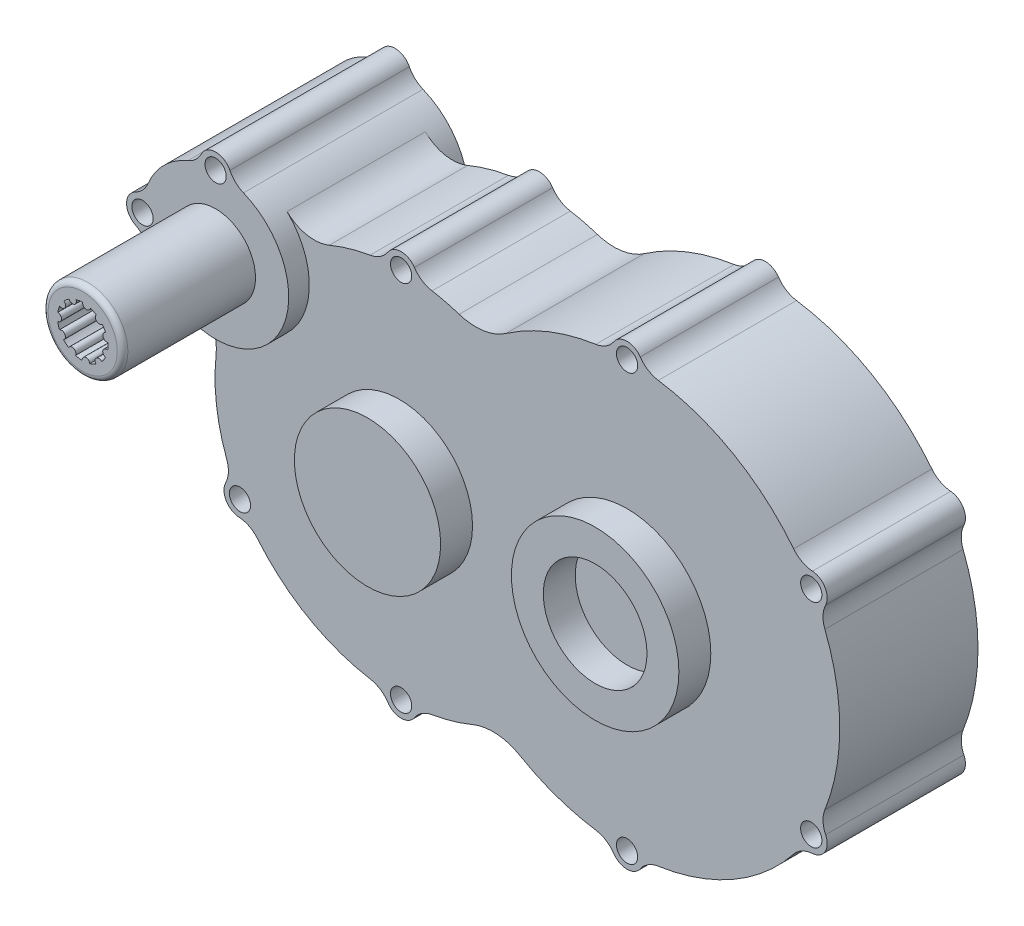
from build123d import *

# Parameters (mm, degrees)
SKETCH1_R           = 4
BOSS_EXTRUDE1_DEPTH = 26
SKETCH1_4_R         = 4
BOSS_EXTRUDE2_DEPTH = 33.75
SKETCH2_R           = 31.5
SKETCH2_R_2         = 19.5
BOSS_EXTRUDE3_DEPTH = 12
BOSS_EXTRUDE4_START = 12
SKETCH3_R           = 31.5
SKETCH3_R_2         = 19.5
BOSS_EXTRUDE4_DEPTH = 12
SKETCH4_R           = 27.5
BOSS_EXTRUDE5_DEPTH = 12
SKETCH5_R           = 27.5
BOSS_EXTRUDE6_DEPTH = 12
SKETCH6_R           = 15
BOSS_EXTRUDE7_DEPTH = 50
CUT_EXTRUDE1_DEPTH  = 35
FILLET2_R           = 2
CUT_EXTRUDE2_DEPTH  = 33
CUT_EXTRUDE3_DEPTH  = 33


with BuildPart() as part:
    # Sketch1 → Boss-Extrude1 (new, symmetric)
    with BuildSketch(Plane.XY):
        with BuildLine():
            ThreePointArc((-58.074376878, -67.913437906), (-49.052816723, -66.422025453), (-40.310336097, -69.101930536))
            ThreePointArc((-40.310336097, -69.101930536), (-26.505925944, -75.481361208), (-11.74374538, -79.133333333))
            ThreePointArc((-11.74374538, -79.133333333), (-7.904816998, -80.549337845), (-4.954392582, -83.384375))
            ThreePointArc((-4.954392582, -83.384375), (0, -86), (4.954392582, -83.384375))
            ThreePointArc((4.954392582, -83.384375), (7.904816998, -80.549337845), (11.74374538, -79.133333333))
            ThreePointArc((11.74374538, -79.133333333), (40, -69.282032303), (62.659604263, -49.737048502))
            ThreePointArc((62.659604263, -49.737048502), (65.805364333, -47.120441255), (69.735790738, -45.982817337))
            ThreePointArc((69.735790738, -45.982817337), (74.478184725, -43), (74.69018332, -37.401557663))
            ThreePointArc((74.69018332, -37.401557663), (73.710181331, -33.42889659), (74.403349643, -29.396284832))
            ThreePointArc((74.403349643, -29.396284832), (80, 0), (74.403349643, 29.396284832))
            ThreePointArc((74.403349643, 29.396284832), (73.710181331, 33.42889659), (74.69018332, 37.401557663))
            ThreePointArc((74.69018332, 37.401557663), (74.478184725, 43), (69.735790738, 45.982817337))
            ThreePointArc((69.735790738, 45.982817337), (65.805364333, 47.120441255), (62.659604263, 49.737048502))
            ThreePointArc((62.659604263, 49.737048502), (40, 69.282032303), (11.74374538, 79.133333333))
            ThreePointArc((11.74374538, 79.133333333), (7.904816998, 80.549337845), (4.954392582, 83.384375))
            ThreePointArc((4.954392582, 83.384375), (0, 86), (-4.954392582, 83.384375))
            ThreePointArc((-4.954392582, 83.384375), (-7.904816998, 80.549337845), (-11.74374538, 79.133333333))
            ThreePointArc((-11.74374538, 79.133333333), (-29.405843417, 74.399572398), (-45.531678193, 65.77891973))
            ThreePointArc((-45.531678193, 65.77891973), (-54.040824443, 62.431190821), (-63.150681694, 63.220722074))
            ThreePointArc((-63.150681694, 63.220722074), (-68.195373584, 64.669123501), (-73.334408157, 65.735475515))
            ThreePointArc((-73.334408157, 65.735475515), (-77.105767385, 67.201828233), (-79.987303798, 70.042618372))
            ThreePointArc((-79.987303798, 70.042618372), (-84.976975529, 72.710475515), (-89.966647259, 70.042618372))
            ThreePointArc((-89.966647259, 70.042618372), (-92.848183673, 67.201828233), (-96.6195429, 65.735475515))
            ThreePointArc((-96.6195429, 65.735475515), (-104.424016511, 63.954899797), (-111.974169426, 61.294928146))
            ThreePointArc((-111.974169426, 61.294928146), (-120.373773229, 60.412501152), (-127.873504081, 64.296578724))
            ThreePointArc((-127.873504081, 64.296578724), (-125.766384192, 27.062122108), (-162.710718585, 21.966941043))
            ThreePointArc((-162.710718585, 21.966941043), (-156.206057813, 14.171994394), (-154.58046116, 4.150555349))
            ThreePointArc((-154.58046116, 4.150555349), (-154.430760535, -12.017167258), (-150.575662711, -27.719265376))
            ThreePointArc((-150.575662711, -27.719265376), (-149.959881802, -31.718534633), (-150.979310022, -35.634413439))
            ThreePointArc((-150.979310022, -35.634413439), (-150.794906216, -41.289524485), (-145.989638292, -44.276778389))
            ThreePointArc((-145.989638292, -44.276778389), (-142.088673658, -45.351867056), (-138.933095339, -47.884783594))
            ThreePointArc((-138.933095339, -47.884783594), (-119.976975529, -63.91130275), (-96.6195429, -72.314524485))
            ThreePointArc((-96.6195429, -72.314524485), (-92.848183673, -73.780877204), (-89.966647259, -76.621667343))
            ThreePointArc((-89.966647259, -76.621667343), (-84.976975529, -79.289524485), (-79.987303798, -76.621667343))
            ThreePointArc((-79.987303798, -76.621667343), (-77.105767385, -73.780877204), (-73.334408157, -72.314524485))
            ThreePointArc((-73.334408157, -72.314524485), (-65.579170326, -70.548168192), (-58.074376878, -67.913437906))
        make_face()
        with Locations(Location((-84.976975529, -73.289524485, 0), (0, 0, 180))):
            Circle(SKETCH1_R, mode=Mode.SUBTRACT)
        with Locations(Location((-145.598753794, -38.289524485, 0), (0, 0, 180))):
            Circle(SKETCH1_R, mode=Mode.SUBTRACT)
        with Locations(Location((0, -80, 0), (0, 0, 180))):
            Circle(SKETCH1_R, mode=Mode.SUBTRACT)
        with Locations(Location((69.282032303, -40, 0), (0, 0, 180))):
            Circle(SKETCH1_R, mode=Mode.SUBTRACT)
        with Locations(Location((-84.976975529, 66.710475515, 0), (0, 0, 180))):
            Circle(SKETCH1_R, mode=Mode.SUBTRACT)
        with Locations(Location((69.282032303, 40, 0), (0, 0, 180))):
            Circle(SKETCH1_R, mode=Mode.SUBTRACT)
        with Locations(Location((0, 80, 0), (0, 0, 180))):
            Circle(SKETCH1_R, mode=Mode.SUBTRACT)
    extrude(amount=BOSS_EXTRUDE1_DEPTH, both=True)

    # Sketch1<4> → Boss-Extrude2 (add, symmetric)
    with BuildSketch(Plane.XY):
        with BuildLine():
            ThreePointArc((-152.365021008, 74.723712774), (-154.497631778, 71.87730603), (-157.491596637, 69.957349137))
            ThreePointArc((-157.491596637, 69.957349137), (-166.445436483, 63.98278562), (-172.42, 55.028945775))
            ThreePointArc((-172.42, 55.028945775), (-174.339956893, 52.034980915), (-177.186363636, 49.902370145))
            ThreePointArc((-177.186363636, 49.902370145), (-180.5, 44.537349137), (-177.186363636, 39.17232813))
            ThreePointArc((-177.186363636, 39.17232813), (-174.339956893, 37.039717359), (-172.42, 34.0457525))
            ThreePointArc((-172.42, 34.0457525), (-127.554563517, 25.091912655), (-136.508403363, 69.957349137))
            ThreePointArc((-136.508403363, 69.957349137), (-139.502368222, 71.87730603), (-141.634978992, 74.723712774))
            ThreePointArc((-141.634978992, 74.723712774), (-147, 78.037349137), (-152.365021008, 74.723712774))
        make_face()
        with Locations((-174.5, 44.537349137)):
            Circle(SKETCH1_4_R, mode=Mode.SUBTRACT)
        with Locations((-147, 72.037349137)):
            Circle(SKETCH1_4_R, mode=Mode.SUBTRACT)
    extrude(amount=BOSS_EXTRUDE2_DEPTH, both=True)

    # Sketch2 → Boss-Extrude3 (add)
    with BuildSketch(Plane.XY.offset(26)):
        Circle(SKETCH2_R)
        Circle(SKETCH2_R_2, mode=Mode.SUBTRACT)
    extrude(amount=BOSS_EXTRUDE3_DEPTH)

    # Sketch3 → Boss-Extrude4 (add)
    with BuildSketch(Plane(origin=(0, 0, -26), x_dir=(-1, 0, 0), z_dir=(0, 0, -1)).offset(BOSS_EXTRUDE4_START)):
        with Locations(Location((0, 0, 0), (0, 0, 180))):
            Circle(SKETCH3_R)
        with Locations(Location((0, 0, 0), (0, 0, 180))):
            Circle(SKETCH3_R_2, mode=Mode.SUBTRACT)
    extrude(amount=-BOSS_EXTRUDE4_DEPTH)

    # Sketch4 → Boss-Extrude5 (add)
    with BuildSketch(Plane.XY.offset(26)):
        with Locations((-85.620743609, -3.228282155)):
            Circle(SKETCH4_R)
    extrude(amount=BOSS_EXTRUDE5_DEPTH)

    # Sketch5 → Boss-Extrude6 (add)
    with BuildSketch(Plane(origin=(0, 0, -26), x_dir=(-1, 0, 0), z_dir=(0, 0, -1))):
        with Locations(Location((85.340023421, -3.78972253, 0), (0, 0, 180))):
            Circle(SKETCH5_R)
    extrude(amount=BOSS_EXTRUDE6_DEPTH)

    # Sketch6 → Boss-Extrude7 (add)
    with BuildSketch(Plane.XY.offset(33.75)):
        with Locations((-147, 44.537349137)):
            Circle(SKETCH6_R)
    extrude(amount=BOSS_EXTRUDE7_DEPTH)

    # Sketch7 → Cut-Extrude1 (cut)
    with BuildSketch(Plane.XY.offset(83.75)):
        with BuildLine():
            ThreePointArc((-155.641503956, 48.483791761), (-156.087714737, 47.305641185), (-156.374108328, 46.078807232))
            ThreePointArc((-156.374108328, 46.078807232), (-154.941981484, 44.617485018), (-156.403303698, 43.185358174))
            ThreePointArc((-156.403303698, 43.185358174), (-156.141723804, 41.952995079), (-155.719376912, 40.766080616))
            ThreePointArc((-155.719376912, 40.766080616), (-153.724544709, 40.311004368), (-154.179620956, 38.316172165))
            ThreePointArc((-154.179620956, 38.316172165), (-153.293300155, 37.420863125), (-152.296304935, 36.650705109))
            ThreePointArc((-152.296304935, 36.650705109), (-150.372112502, 37.346358321), (-149.67645929, 35.422165888))
            ThreePointArc((-149.67645929, 35.422165888), (-148.446798174, 35.148165198), (-147.191693563, 35.039283356))
            ThreePointArc((-147.191693563, 35.039283356), (-145.949058402, 36.664801049), (-144.32354071, 35.422165888))
            ThreePointArc((-144.32354071, 35.422165888), (-143.140947995, 35.856466831), (-142.026220839, 36.443430379))
            ThreePointArc((-142.026220839, 36.443430379), (-141.859670834, 38.48272217), (-139.820379044, 38.316172165))
            ThreePointArc((-139.820379044, 38.316172165), (-139.060319561, 39.320887259), (-138.439887856, 40.417339419))
            ThreePointArc((-138.439887856, 40.417339419), (-139.402301456, 42.222944573), (-137.596696302, 43.185358174))
            ThreePointArc((-137.596696302, 43.185358174), (-137.500483567, 44.441497477), (-137.571329995, 45.699322434))
            ThreePointArc((-137.571329995, 45.699322434), (-139.357147683, 46.697974073), (-138.358496044, 48.483791761))
            ThreePointArc((-138.358496044, 48.483791761), (-138.95667692, 49.592539919), (-139.696308241, 50.612387137))
            ThreePointArc((-139.696308241, 50.612387137), (-141.738545519, 50.487020422), (-141.863912234, 52.529257699))
            ThreePointArc((-141.863912234, 52.529257699), (-142.96656852, 53.138595006), (-144.140157016, 53.596670199))
            ThreePointArc((-144.140157016, 53.596670199), (-145.790417977, 52.387088176), (-147, 54.037349137))
            ThreePointArc((-147, 54.037349137), (-148.257046116, 53.953815304), (-149.491985731, 53.704682835))
            ThreePointArc((-149.491985731, 53.704682835), (-150.22632418, 51.794919249), (-152.136087766, 52.529257699))
            ThreePointArc((-152.136087766, 52.529257699), (-153.148420452, 51.779374127), (-154.052626584, 50.902131794))
            ThreePointArc((-154.052626584, 50.902131794), (-153.637895253, 48.898523091), (-155.641503956, 48.483791761))
        make_face()
    extrude(amount=-CUT_EXTRUDE1_DEPTH, mode=Mode.SUBTRACT)

    # Fillet2
    fillet2_edges = [part.edges().sort_by_distance(p)[0] for p in [
        (-162, 44.537349137, 83.75),
    ]]
    fillet(fillet2_edges, radius=FILLET2_R)

    # Sketch9 → Cut-Extrude2 (cut)
    with BuildSketch(Plane.XY.offset(71)):
        with BuildLine():
            Line((0, 12), (0, 10.798193828))
            ThreePointArc((0, 10.798193828), (-0.942152662, 10.757013447), (-1.877119269, 10.6337864))
            Line((-1.877119269, 10.6337864), (-2.318777751, 11.773838361))
            Line((-2.318777751, 11.773838361), (-4.334899994, 11.189666753))
            Line((-4.334899994, 11.189666753), (-3.90075753, 10.069015872))
            ThreePointArc((-3.90075753, 10.069015872), (-4.764412654, 9.690271514), (-5.591728307, 9.237616819))
            Line((-5.591728307, 9.237616819), (-6.415396846, 10.141138166))
            Line((-6.415396846, 10.141138166), (-8.084347724, 8.868107007))
            Line((-8.084347724, 8.868107007), (-7.274696141, 7.979961529))
            ThreePointArc((-7.274696141, 7.979961529), (-7.943212317, 7.314804716), (-8.551143451, 6.593855899))
            Line((-8.551143451, 6.593855899), (-9.645581048, 7.138821069))
            Line((-9.645581048, 7.138821069), (-10.741959496, 5.348860269))
            Line((-10.741959496, 5.348860269), (-9.666146728, 4.813169162))
            ThreePointArc((-9.666146728, 4.813169162), (-10.049237141, 3.951433009), (-10.35567929, 3.059558203))
            Line((-10.35567929, 3.059558203), (-11.573076081, 3.172366628))
            Line((-11.573076081, 3.172366628), (-11.948810116, 1.107220314))
            Line((-11.948810116, 1.107220314), (-10.752130637, 0.99633163))
            ThreePointArc((-10.752130637, 0.99633163), (-10.798056805, 0.054398379), (-10.761623257, -0.887949783))
            Line((-10.761623257, -0.887949783), (-11.937563061, -1.222533504))
            Line((-11.937563061, -1.222533504), (-11.541907718, -3.283955881))
            Line((-11.541907718, -3.283955881), (-10.385979724, -2.95506601))
            ThreePointArc((-10.385979724, -2.95506601), (-10.088539063, -3.849983054), (-9.714150372, -4.71553523))
            Line((-9.714150372, -4.71553523), (-10.689816001, -5.452323713))
            Line((-10.689816001, -5.452323713), (-9.576206727, -7.231615637))
            Line((-9.576206727, -7.231615637), (-8.617144698, -6.507365611))
            ThreePointArc((-8.617144698, -6.507365611), (-8.016508218, -7.234402942), (-7.35472765, -7.906261515))
            Line((-7.35472765, -7.906261515), (-7.998350056, -8.945747391))
            Line((-7.998350056, -8.945747391), (-6.317185955, -10.202605629))
            Line((-6.317185955, -10.202605629), (-5.684516532, -9.180809427))
            ThreePointArc((-5.684516532, -9.180809427), (-4.861803518, -9.641776626), (-4.002008206, -10.029203372))
            Line((-4.002008206, -10.029203372), (-4.226662615, -11.230998314))
            Line((-4.226662615, -11.230998314), (-2.204994214, -11.795677196))
            Line((-2.204994214, -11.795677196), (-1.984162909, -10.614334058))
            ThreePointArc((-1.984162909, -10.614334058), (-1.050485312, -10.746974949), (-0.108795377, -10.797645739))
            Line((-0.108795377, -10.797645739), (0.115859032, -11.999440682))
            Line((0.115859032, -11.999440682), (2.204994214, -11.795677196))
            Line((2.204994214, -11.795677196), (1.984162909, -10.614334058))
            ThreePointArc((1.984162909, -10.614334058), (2.902706756, -10.400734754), (3.79911087, -10.107806218))
            Line((3.79911087, -10.107806218), (4.442733275, -11.147292095))
            Line((4.442733275, -11.147292095), (6.317185955, -10.202605629))
            Line((6.317185955, -10.202605629), (5.684516532, -9.180809427))
            ThreePointArc((5.684516532, -9.180809427), (6.463872193, -8.649817699), (7.193926142, -8.052851458))
            Line((7.193926142, -8.052851458), (8.169591772, -8.789639941))
            Line((8.169591772, -8.789639941), (9.576206727, -7.231615637))
            Line((9.576206727, -7.231615637), (8.617144698, -6.507365611))
            ThreePointArc((8.617144698, -6.507365611), (9.152055872, -5.730694833), (9.617161826, -4.910314486))
            Line((9.617161826, -4.910314486), (10.79310163, -5.244898207))
            Line((10.79310163, -5.244898207), (11.541907718, -3.283955881))
            Line((11.541907718, -3.283955881), (10.385979724, -2.95506601))
            ThreePointArc((10.385979724, -2.95506601), (10.604203692, -2.037609874), (10.741546515, -1.104612334))
            Line((10.741546515, -1.104612334), (11.958943306, -0.991803908))
            Line((11.958943306, -0.991803908), (11.948810116, 1.107220314))
            Line((11.948810116, 1.107220314), (10.752130637, 0.99633163))
            ThreePointArc((10.752130637, 0.99633163), (10.624195044, 1.930665588), (10.415225826, 2.850273835))
            Line((10.415225826, 2.850273835), (11.509663423, 3.395239004))
            Line((11.509663423, 3.395239004), (10.741959496, 5.348860269))
            Line((10.741959496, 5.348860269), (9.666146728, 4.813169162))
            ThreePointArc((9.666146728, 4.813169162), (9.209329984, 5.638193965), (8.682271177, 6.420214729))
            Line((8.682271177, 6.420214729), (9.505939716, 7.323736076))
            Line((9.505939716, 7.323736076), (8.084347724, 8.868107007))
            Line((8.084347724, 8.868107007), (7.274696141, 7.979961529))
            ThreePointArc((7.274696141, 7.979961529), (6.55069388, 8.584253004), (5.776727695, 9.123070047))
            Line((5.776727695, 9.123070047), (6.218386177, 10.263122008))
            Line((6.218386177, 10.263122008), (4.334899994, 11.189666753))
            Line((4.334899994, 11.189666753), (3.90075753, 10.069015872))
            ThreePointArc((3.90075753, 10.069015872), (3.007350268, 10.370961108), (2.091005127, 10.593804204))
            Line((2.091005127, 10.593804204), (2.091005127, 11.816416443))
            Line((2.091005127, 11.816416443), (0, 12))
        make_face()
        with BuildLine():
            Line((0, 12), (0, 10.798193828))
            ThreePointArc((0, 10.798193828), (-0.942152662, 10.757013447), (-1.877119269, 10.6337864))
            Line((-1.877119269, 10.6337864), (-2.318777751, 11.773838361))
            Line((-2.318777751, 11.773838361), (-4.334899994, 11.189666753))
            Line((-4.334899994, 11.189666753), (-3.90075753, 10.069015872))
            ThreePointArc((-3.90075753, 10.069015872), (-4.764412654, 9.690271514), (-5.591728307, 9.237616819))
            Line((-5.591728307, 9.237616819), (-6.415396846, 10.141138166))
            Line((-6.415396846, 10.141138166), (-8.084347724, 8.868107007))
            Line((-8.084347724, 8.868107007), (-7.274696141, 7.979961529))
            ThreePointArc((-7.274696141, 7.979961529), (-7.943212317, 7.314804716), (-8.551143451, 6.593855899))
            Line((-8.551143451, 6.593855899), (-9.645581048, 7.138821069))
            Line((-9.645581048, 7.138821069), (-10.741959496, 5.348860269))
            Line((-10.741959496, 5.348860269), (-9.666146728, 4.813169162))
            ThreePointArc((-9.666146728, 4.813169162), (-10.049237141, 3.951433009), (-10.35567929, 3.059558203))
            Line((-10.35567929, 3.059558203), (-11.573076081, 3.172366628))
            Line((-11.573076081, 3.172366628), (-11.948810116, 1.107220314))
            Line((-11.948810116, 1.107220314), (-10.752130637, 0.99633163))
            ThreePointArc((-10.752130637, 0.99633163), (-10.798056805, 0.054398379), (-10.761623257, -0.887949783))
            Line((-10.761623257, -0.887949783), (-11.937563061, -1.222533504))
            Line((-11.937563061, -1.222533504), (-11.541907718, -3.283955881))
            Line((-11.541907718, -3.283955881), (-10.385979724, -2.95506601))
            ThreePointArc((-10.385979724, -2.95506601), (-10.088539063, -3.849983054), (-9.714150372, -4.71553523))
            Line((-9.714150372, -4.71553523), (-10.689816001, -5.452323713))
            Line((-10.689816001, -5.452323713), (-9.576206727, -7.231615637))
            Line((-9.576206727, -7.231615637), (-8.617144698, -6.507365611))
            ThreePointArc((-8.617144698, -6.507365611), (-8.016508218, -7.234402942), (-7.35472765, -7.906261515))
            Line((-7.35472765, -7.906261515), (-7.998350056, -8.945747391))
            Line((-7.998350056, -8.945747391), (-6.317185955, -10.202605629))
            Line((-6.317185955, -10.202605629), (-5.684516532, -9.180809427))
            ThreePointArc((-5.684516532, -9.180809427), (-4.861803518, -9.641776626), (-4.002008206, -10.029203372))
            Line((-4.002008206, -10.029203372), (-4.226662615, -11.230998314))
            Line((-4.226662615, -11.230998314), (-2.204994214, -11.795677196))
            Line((-2.204994214, -11.795677196), (-1.984162909, -10.614334058))
            ThreePointArc((-1.984162909, -10.614334058), (-1.050485312, -10.746974949), (-0.108795377, -10.797645739))
            Line((-0.108795377, -10.797645739), (0.115859032, -11.999440682))
            Line((0.115859032, -11.999440682), (2.204994214, -11.795677196))
            Line((2.204994214, -11.795677196), (1.984162909, -10.614334058))
            ThreePointArc((1.984162909, -10.614334058), (2.902706756, -10.400734754), (3.79911087, -10.107806218))
            Line((3.79911087, -10.107806218), (4.442733275, -11.147292095))
            Line((4.442733275, -11.147292095), (6.317185955, -10.202605629))
            Line((6.317185955, -10.202605629), (5.684516532, -9.180809427))
            ThreePointArc((5.684516532, -9.180809427), (6.463872193, -8.649817699), (7.193926142, -8.052851458))
            Line((7.193926142, -8.052851458), (8.169591772, -8.789639941))
            Line((8.169591772, -8.789639941), (9.576206727, -7.231615637))
            Line((9.576206727, -7.231615637), (8.617144698, -6.507365611))
            ThreePointArc((8.617144698, -6.507365611), (9.152055872, -5.730694833), (9.617161826, -4.910314486))
            Line((9.617161826, -4.910314486), (10.79310163, -5.244898207))
            Line((10.79310163, -5.244898207), (11.541907718, -3.283955881))
            Line((11.541907718, -3.283955881), (10.385979724, -2.95506601))
            ThreePointArc((10.385979724, -2.95506601), (10.604203692, -2.037609874), (10.741546515, -1.104612334))
            Line((10.741546515, -1.104612334), (11.958943306, -0.991803908))
            Line((11.958943306, -0.991803908), (11.948810116, 1.107220314))
            Line((11.948810116, 1.107220314), (10.752130637, 0.99633163))
            ThreePointArc((10.752130637, 0.99633163), (10.624195044, 1.930665588), (10.415225826, 2.850273835))
            Line((10.415225826, 2.850273835), (11.509663423, 3.395239004))
            Line((11.509663423, 3.395239004), (10.741959496, 5.348860269))
            Line((10.741959496, 5.348860269), (9.666146728, 4.813169162))
            ThreePointArc((9.666146728, 4.813169162), (9.209329984, 5.638193965), (8.682271177, 6.420214729))
            Line((8.682271177, 6.420214729), (9.505939716, 7.323736076))
            Line((9.505939716, 7.323736076), (8.084347724, 8.868107007))
            Line((8.084347724, 8.868107007), (7.274696141, 7.979961529))
            ThreePointArc((7.274696141, 7.979961529), (6.55069388, 8.584253004), (5.776727695, 9.123070047))
            Line((5.776727695, 9.123070047), (6.218386177, 10.263122008))
            Line((6.218386177, 10.263122008), (4.334899994, 11.189666753))
            Line((4.334899994, 11.189666753), (3.90075753, 10.069015872))
            ThreePointArc((3.90075753, 10.069015872), (3.007350268, 10.370961108), (2.091005127, 10.593804204))
            Line((2.091005127, 10.593804204), (2.091005127, 11.816416443))
            Line((2.091005127, 11.816416443), (0, 12))
        make_face()
        with BuildLine():
            Line((0, 12), (0, 10.798193828))
            ThreePointArc((0, 10.798193828), (-0.942152662, 10.757013447), (-1.877119269, 10.6337864))
            Line((-1.877119269, 10.6337864), (-2.318777751, 11.773838361))
            Line((-2.318777751, 11.773838361), (-4.334899994, 11.189666753))
            Line((-4.334899994, 11.189666753), (-3.90075753, 10.069015872))
            ThreePointArc((-3.90075753, 10.069015872), (-4.764412654, 9.690271514), (-5.591728307, 9.237616819))
            Line((-5.591728307, 9.237616819), (-6.415396846, 10.141138166))
            Line((-6.415396846, 10.141138166), (-8.084347724, 8.868107007))
            Line((-8.084347724, 8.868107007), (-7.274696141, 7.979961529))
            ThreePointArc((-7.274696141, 7.979961529), (-7.943212317, 7.314804716), (-8.551143451, 6.593855899))
            Line((-8.551143451, 6.593855899), (-9.645581048, 7.138821069))
            Line((-9.645581048, 7.138821069), (-10.741959496, 5.348860269))
            Line((-10.741959496, 5.348860269), (-9.666146728, 4.813169162))
            ThreePointArc((-9.666146728, 4.813169162), (-10.049237141, 3.951433009), (-10.35567929, 3.059558203))
            Line((-10.35567929, 3.059558203), (-11.573076081, 3.172366628))
            Line((-11.573076081, 3.172366628), (-11.948810116, 1.107220314))
            Line((-11.948810116, 1.107220314), (-10.752130637, 0.99633163))
            ThreePointArc((-10.752130637, 0.99633163), (-10.798056805, 0.054398379), (-10.761623257, -0.887949783))
            Line((-10.761623257, -0.887949783), (-11.937563061, -1.222533504))
            Line((-11.937563061, -1.222533504), (-11.541907718, -3.283955881))
            Line((-11.541907718, -3.283955881), (-10.385979724, -2.95506601))
            ThreePointArc((-10.385979724, -2.95506601), (-10.088539063, -3.849983054), (-9.714150372, -4.71553523))
            Line((-9.714150372, -4.71553523), (-10.689816001, -5.452323713))
            Line((-10.689816001, -5.452323713), (-9.576206727, -7.231615637))
            Line((-9.576206727, -7.231615637), (-8.617144698, -6.507365611))
            ThreePointArc((-8.617144698, -6.507365611), (-8.016508218, -7.234402942), (-7.35472765, -7.906261515))
            Line((-7.35472765, -7.906261515), (-7.998350056, -8.945747391))
            Line((-7.998350056, -8.945747391), (-6.317185955, -10.202605629))
            Line((-6.317185955, -10.202605629), (-5.684516532, -9.180809427))
            ThreePointArc((-5.684516532, -9.180809427), (-4.861803518, -9.641776626), (-4.002008206, -10.029203372))
            Line((-4.002008206, -10.029203372), (-4.226662615, -11.230998314))
            Line((-4.226662615, -11.230998314), (-2.204994214, -11.795677196))
            Line((-2.204994214, -11.795677196), (-1.984162909, -10.614334058))
            ThreePointArc((-1.984162909, -10.614334058), (-1.050485312, -10.746974949), (-0.108795377, -10.797645739))
            Line((-0.108795377, -10.797645739), (0.115859032, -11.999440682))
            Line((0.115859032, -11.999440682), (2.204994214, -11.795677196))
            Line((2.204994214, -11.795677196), (1.984162909, -10.614334058))
            ThreePointArc((1.984162909, -10.614334058), (2.902706756, -10.400734754), (3.79911087, -10.107806218))
            Line((3.79911087, -10.107806218), (4.442733275, -11.147292095))
            Line((4.442733275, -11.147292095), (6.317185955, -10.202605629))
            Line((6.317185955, -10.202605629), (5.684516532, -9.180809427))
            ThreePointArc((5.684516532, -9.180809427), (6.463872193, -8.649817699), (7.193926142, -8.052851458))
            Line((7.193926142, -8.052851458), (8.169591772, -8.789639941))
            Line((8.169591772, -8.789639941), (9.576206727, -7.231615637))
            Line((9.576206727, -7.231615637), (8.617144698, -6.507365611))
            ThreePointArc((8.617144698, -6.507365611), (9.152055872, -5.730694833), (9.617161826, -4.910314486))
            Line((9.617161826, -4.910314486), (10.79310163, -5.244898207))
            Line((10.79310163, -5.244898207), (11.541907718, -3.283955881))
            Line((11.541907718, -3.283955881), (10.385979724, -2.95506601))
            ThreePointArc((10.385979724, -2.95506601), (10.604203692, -2.037609874), (10.741546515, -1.104612334))
            Line((10.741546515, -1.104612334), (11.958943306, -0.991803908))
            Line((11.958943306, -0.991803908), (11.948810116, 1.107220314))
            Line((11.948810116, 1.107220314), (10.752130637, 0.99633163))
            ThreePointArc((10.752130637, 0.99633163), (10.624195044, 1.930665588), (10.415225826, 2.850273835))
            Line((10.415225826, 2.850273835), (11.509663423, 3.395239004))
            Line((11.509663423, 3.395239004), (10.741959496, 5.348860269))
            Line((10.741959496, 5.348860269), (9.666146728, 4.813169162))
            ThreePointArc((9.666146728, 4.813169162), (9.209329984, 5.638193965), (8.682271177, 6.420214729))
            Line((8.682271177, 6.420214729), (9.505939716, 7.323736076))
            Line((9.505939716, 7.323736076), (8.084347724, 8.868107007))
            Line((8.084347724, 8.868107007), (7.274696141, 7.979961529))
            ThreePointArc((7.274696141, 7.979961529), (6.55069388, 8.584253004), (5.776727695, 9.123070047))
            Line((5.776727695, 9.123070047), (6.218386177, 10.263122008))
            Line((6.218386177, 10.263122008), (4.334899994, 11.189666753))
            Line((4.334899994, 11.189666753), (3.90075753, 10.069015872))
            ThreePointArc((3.90075753, 10.069015872), (3.007350268, 10.370961108), (2.091005127, 10.593804204))
            Line((2.091005127, 10.593804204), (2.091005127, 11.816416443))
            Line((2.091005127, 11.816416443), (0, 12))
        make_face()
        with BuildLine():
            Line((0, 12), (0, 10.798193828))
            ThreePointArc((0, 10.798193828), (-0.942152662, 10.757013447), (-1.877119269, 10.6337864))
            Line((-1.877119269, 10.6337864), (-2.318777751, 11.773838361))
            Line((-2.318777751, 11.773838361), (-4.334899994, 11.189666753))
            Line((-4.334899994, 11.189666753), (-3.90075753, 10.069015872))
            ThreePointArc((-3.90075753, 10.069015872), (-4.764412654, 9.690271514), (-5.591728307, 9.237616819))
            Line((-5.591728307, 9.237616819), (-6.415396846, 10.141138166))
            Line((-6.415396846, 10.141138166), (-8.084347724, 8.868107007))
            Line((-8.084347724, 8.868107007), (-7.274696141, 7.979961529))
            ThreePointArc((-7.274696141, 7.979961529), (-7.943212317, 7.314804716), (-8.551143451, 6.593855899))
            Line((-8.551143451, 6.593855899), (-9.645581048, 7.138821069))
            Line((-9.645581048, 7.138821069), (-10.741959496, 5.348860269))
            Line((-10.741959496, 5.348860269), (-9.666146728, 4.813169162))
            ThreePointArc((-9.666146728, 4.813169162), (-10.049237141, 3.951433009), (-10.35567929, 3.059558203))
            Line((-10.35567929, 3.059558203), (-11.573076081, 3.172366628))
            Line((-11.573076081, 3.172366628), (-11.948810116, 1.107220314))
            Line((-11.948810116, 1.107220314), (-10.752130637, 0.99633163))
            ThreePointArc((-10.752130637, 0.99633163), (-10.798056805, 0.054398379), (-10.761623257, -0.887949783))
            Line((-10.761623257, -0.887949783), (-11.937563061, -1.222533504))
            Line((-11.937563061, -1.222533504), (-11.541907718, -3.283955881))
            Line((-11.541907718, -3.283955881), (-10.385979724, -2.95506601))
            ThreePointArc((-10.385979724, -2.95506601), (-10.088539063, -3.849983054), (-9.714150372, -4.71553523))
            Line((-9.714150372, -4.71553523), (-10.689816001, -5.452323713))
            Line((-10.689816001, -5.452323713), (-9.576206727, -7.231615637))
            Line((-9.576206727, -7.231615637), (-8.617144698, -6.507365611))
            ThreePointArc((-8.617144698, -6.507365611), (-8.016508218, -7.234402942), (-7.35472765, -7.906261515))
            Line((-7.35472765, -7.906261515), (-7.998350056, -8.945747391))
            Line((-7.998350056, -8.945747391), (-6.317185955, -10.202605629))
            Line((-6.317185955, -10.202605629), (-5.684516532, -9.180809427))
            ThreePointArc((-5.684516532, -9.180809427), (-4.861803518, -9.641776626), (-4.002008206, -10.029203372))
            Line((-4.002008206, -10.029203372), (-4.226662615, -11.230998314))
            Line((-4.226662615, -11.230998314), (-2.204994214, -11.795677196))
            Line((-2.204994214, -11.795677196), (-1.984162909, -10.614334058))
            ThreePointArc((-1.984162909, -10.614334058), (-1.050485312, -10.746974949), (-0.108795377, -10.797645739))
            Line((-0.108795377, -10.797645739), (0.115859032, -11.999440682))
            Line((0.115859032, -11.999440682), (2.204994214, -11.795677196))
            Line((2.204994214, -11.795677196), (1.984162909, -10.614334058))
            ThreePointArc((1.984162909, -10.614334058), (2.902706756, -10.400734754), (3.79911087, -10.107806218))
            Line((3.79911087, -10.107806218), (4.442733275, -11.147292095))
            Line((4.442733275, -11.147292095), (6.317185955, -10.202605629))
            Line((6.317185955, -10.202605629), (5.684516532, -9.180809427))
            ThreePointArc((5.684516532, -9.180809427), (6.463872193, -8.649817699), (7.193926142, -8.052851458))
            Line((7.193926142, -8.052851458), (8.169591772, -8.789639941))
            Line((8.169591772, -8.789639941), (9.576206727, -7.231615637))
            Line((9.576206727, -7.231615637), (8.617144698, -6.507365611))
            ThreePointArc((8.617144698, -6.507365611), (9.152055872, -5.730694833), (9.617161826, -4.910314486))
            Line((9.617161826, -4.910314486), (10.79310163, -5.244898207))
            Line((10.79310163, -5.244898207), (11.541907718, -3.283955881))
            Line((11.541907718, -3.283955881), (10.385979724, -2.95506601))
            ThreePointArc((10.385979724, -2.95506601), (10.604203692, -2.037609874), (10.741546515, -1.104612334))
            Line((10.741546515, -1.104612334), (11.958943306, -0.991803908))
            Line((11.958943306, -0.991803908), (11.948810116, 1.107220314))
            Line((11.948810116, 1.107220314), (10.752130637, 0.99633163))
            ThreePointArc((10.752130637, 0.99633163), (10.624195044, 1.930665588), (10.415225826, 2.850273835))
            Line((10.415225826, 2.850273835), (11.509663423, 3.395239004))
            Line((11.509663423, 3.395239004), (10.741959496, 5.348860269))
            Line((10.741959496, 5.348860269), (9.666146728, 4.813169162))
            ThreePointArc((9.666146728, 4.813169162), (9.209329984, 5.638193965), (8.682271177, 6.420214729))
            Line((8.682271177, 6.420214729), (9.505939716, 7.323736076))
            Line((9.505939716, 7.323736076), (8.084347724, 8.868107007))
            Line((8.084347724, 8.868107007), (7.274696141, 7.979961529))
            ThreePointArc((7.274696141, 7.979961529), (6.55069388, 8.584253004), (5.776727695, 9.123070047))
            Line((5.776727695, 9.123070047), (6.218386177, 10.263122008))
            Line((6.218386177, 10.263122008), (4.334899994, 11.189666753))
            Line((4.334899994, 11.189666753), (3.90075753, 10.069015872))
            ThreePointArc((3.90075753, 10.069015872), (3.007350268, 10.370961108), (2.091005127, 10.593804204))
            Line((2.091005127, 10.593804204), (2.091005127, 11.816416443))
            Line((2.091005127, 11.816416443), (0, 12))
        make_face()
        with BuildLine():
            Line((0, 12), (0, 10.798193828))
            ThreePointArc((0, 10.798193828), (-0.942152662, 10.757013447), (-1.877119269, 10.6337864))
            Line((-1.877119269, 10.6337864), (-2.318777751, 11.773838361))
            Line((-2.318777751, 11.773838361), (-4.334899994, 11.189666753))
            Line((-4.334899994, 11.189666753), (-3.90075753, 10.069015872))
            ThreePointArc((-3.90075753, 10.069015872), (-4.764412654, 9.690271514), (-5.591728307, 9.237616819))
            Line((-5.591728307, 9.237616819), (-6.415396846, 10.141138166))
            Line((-6.415396846, 10.141138166), (-8.084347724, 8.868107007))
            Line((-8.084347724, 8.868107007), (-7.274696141, 7.979961529))
            ThreePointArc((-7.274696141, 7.979961529), (-7.943212317, 7.314804716), (-8.551143451, 6.593855899))
            Line((-8.551143451, 6.593855899), (-9.645581048, 7.138821069))
            Line((-9.645581048, 7.138821069), (-10.741959496, 5.348860269))
            Line((-10.741959496, 5.348860269), (-9.666146728, 4.813169162))
            ThreePointArc((-9.666146728, 4.813169162), (-10.049237141, 3.951433009), (-10.35567929, 3.059558203))
            Line((-10.35567929, 3.059558203), (-11.573076081, 3.172366628))
            Line((-11.573076081, 3.172366628), (-11.948810116, 1.107220314))
            Line((-11.948810116, 1.107220314), (-10.752130637, 0.99633163))
            ThreePointArc((-10.752130637, 0.99633163), (-10.798056805, 0.054398379), (-10.761623257, -0.887949783))
            Line((-10.761623257, -0.887949783), (-11.937563061, -1.222533504))
            Line((-11.937563061, -1.222533504), (-11.541907718, -3.283955881))
            Line((-11.541907718, -3.283955881), (-10.385979724, -2.95506601))
            ThreePointArc((-10.385979724, -2.95506601), (-10.088539063, -3.849983054), (-9.714150372, -4.71553523))
            Line((-9.714150372, -4.71553523), (-10.689816001, -5.452323713))
            Line((-10.689816001, -5.452323713), (-9.576206727, -7.231615637))
            Line((-9.576206727, -7.231615637), (-8.617144698, -6.507365611))
            ThreePointArc((-8.617144698, -6.507365611), (-8.016508218, -7.234402942), (-7.35472765, -7.906261515))
            Line((-7.35472765, -7.906261515), (-7.998350056, -8.945747391))
            Line((-7.998350056, -8.945747391), (-6.317185955, -10.202605629))
            Line((-6.317185955, -10.202605629), (-5.684516532, -9.180809427))
            ThreePointArc((-5.684516532, -9.180809427), (-4.861803518, -9.641776626), (-4.002008206, -10.029203372))
            Line((-4.002008206, -10.029203372), (-4.226662615, -11.230998314))
            Line((-4.226662615, -11.230998314), (-2.204994214, -11.795677196))
            Line((-2.204994214, -11.795677196), (-1.984162909, -10.614334058))
            ThreePointArc((-1.984162909, -10.614334058), (-1.050485312, -10.746974949), (-0.108795377, -10.797645739))
            Line((-0.108795377, -10.797645739), (0.115859032, -11.999440682))
            Line((0.115859032, -11.999440682), (2.204994214, -11.795677196))
            Line((2.204994214, -11.795677196), (1.984162909, -10.614334058))
            ThreePointArc((1.984162909, -10.614334058), (2.902706756, -10.400734754), (3.79911087, -10.107806218))
            Line((3.79911087, -10.107806218), (4.442733275, -11.147292095))
            Line((4.442733275, -11.147292095), (6.317185955, -10.202605629))
            Line((6.317185955, -10.202605629), (5.684516532, -9.180809427))
            ThreePointArc((5.684516532, -9.180809427), (6.463872193, -8.649817699), (7.193926142, -8.052851458))
            Line((7.193926142, -8.052851458), (8.169591772, -8.789639941))
            Line((8.169591772, -8.789639941), (9.576206727, -7.231615637))
            Line((9.576206727, -7.231615637), (8.617144698, -6.507365611))
            ThreePointArc((8.617144698, -6.507365611), (9.152055872, -5.730694833), (9.617161826, -4.910314486))
            Line((9.617161826, -4.910314486), (10.79310163, -5.244898207))
            Line((10.79310163, -5.244898207), (11.541907718, -3.283955881))
            Line((11.541907718, -3.283955881), (10.385979724, -2.95506601))
            ThreePointArc((10.385979724, -2.95506601), (10.604203692, -2.037609874), (10.741546515, -1.104612334))
            Line((10.741546515, -1.104612334), (11.958943306, -0.991803908))
            Line((11.958943306, -0.991803908), (11.948810116, 1.107220314))
            Line((11.948810116, 1.107220314), (10.752130637, 0.99633163))
            ThreePointArc((10.752130637, 0.99633163), (10.624195044, 1.930665588), (10.415225826, 2.850273835))
            Line((10.415225826, 2.850273835), (11.509663423, 3.395239004))
            Line((11.509663423, 3.395239004), (10.741959496, 5.348860269))
            Line((10.741959496, 5.348860269), (9.666146728, 4.813169162))
            ThreePointArc((9.666146728, 4.813169162), (9.209329984, 5.638193965), (8.682271177, 6.420214729))
            Line((8.682271177, 6.420214729), (9.505939716, 7.323736076))
            Line((9.505939716, 7.323736076), (8.084347724, 8.868107007))
            Line((8.084347724, 8.868107007), (7.274696141, 7.979961529))
            ThreePointArc((7.274696141, 7.979961529), (6.55069388, 8.584253004), (5.776727695, 9.123070047))
            Line((5.776727695, 9.123070047), (6.218386177, 10.263122008))
            Line((6.218386177, 10.263122008), (4.334899994, 11.189666753))
            Line((4.334899994, 11.189666753), (3.90075753, 10.069015872))
            ThreePointArc((3.90075753, 10.069015872), (3.007350268, 10.370961108), (2.091005127, 10.593804204))
            Line((2.091005127, 10.593804204), (2.091005127, 11.816416443))
            Line((2.091005127, 11.816416443), (0, 12))
        make_face()
        with BuildLine():
            Line((0, 12), (0, 10.798193828))
            ThreePointArc((0, 10.798193828), (-0.942152662, 10.757013447), (-1.877119269, 10.6337864))
            Line((-1.877119269, 10.6337864), (-2.318777751, 11.773838361))
            Line((-2.318777751, 11.773838361), (-4.334899994, 11.189666753))
            Line((-4.334899994, 11.189666753), (-3.90075753, 10.069015872))
            ThreePointArc((-3.90075753, 10.069015872), (-4.764412654, 9.690271514), (-5.591728307, 9.237616819))
            Line((-5.591728307, 9.237616819), (-6.415396846, 10.141138166))
            Line((-6.415396846, 10.141138166), (-8.084347724, 8.868107007))
            Line((-8.084347724, 8.868107007), (-7.274696141, 7.979961529))
            ThreePointArc((-7.274696141, 7.979961529), (-7.943212317, 7.314804716), (-8.551143451, 6.593855899))
            Line((-8.551143451, 6.593855899), (-9.645581048, 7.138821069))
            Line((-9.645581048, 7.138821069), (-10.741959496, 5.348860269))
            Line((-10.741959496, 5.348860269), (-9.666146728, 4.813169162))
            ThreePointArc((-9.666146728, 4.813169162), (-10.049237141, 3.951433009), (-10.35567929, 3.059558203))
            Line((-10.35567929, 3.059558203), (-11.573076081, 3.172366628))
            Line((-11.573076081, 3.172366628), (-11.948810116, 1.107220314))
            Line((-11.948810116, 1.107220314), (-10.752130637, 0.99633163))
            ThreePointArc((-10.752130637, 0.99633163), (-10.798056805, 0.054398379), (-10.761623257, -0.887949783))
            Line((-10.761623257, -0.887949783), (-11.937563061, -1.222533504))
            Line((-11.937563061, -1.222533504), (-11.541907718, -3.283955881))
            Line((-11.541907718, -3.283955881), (-10.385979724, -2.95506601))
            ThreePointArc((-10.385979724, -2.95506601), (-10.088539063, -3.849983054), (-9.714150372, -4.71553523))
            Line((-9.714150372, -4.71553523), (-10.689816001, -5.452323713))
            Line((-10.689816001, -5.452323713), (-9.576206727, -7.231615637))
            Line((-9.576206727, -7.231615637), (-8.617144698, -6.507365611))
            ThreePointArc((-8.617144698, -6.507365611), (-8.016508218, -7.234402942), (-7.35472765, -7.906261515))
            Line((-7.35472765, -7.906261515), (-7.998350056, -8.945747391))
            Line((-7.998350056, -8.945747391), (-6.317185955, -10.202605629))
            Line((-6.317185955, -10.202605629), (-5.684516532, -9.180809427))
            ThreePointArc((-5.684516532, -9.180809427), (-4.861803518, -9.641776626), (-4.002008206, -10.029203372))
            Line((-4.002008206, -10.029203372), (-4.226662615, -11.230998314))
            Line((-4.226662615, -11.230998314), (-2.204994214, -11.795677196))
            Line((-2.204994214, -11.795677196), (-1.984162909, -10.614334058))
            ThreePointArc((-1.984162909, -10.614334058), (-1.050485312, -10.746974949), (-0.108795377, -10.797645739))
            Line((-0.108795377, -10.797645739), (0.115859032, -11.999440682))
            Line((0.115859032, -11.999440682), (2.204994214, -11.795677196))
            Line((2.204994214, -11.795677196), (1.984162909, -10.614334058))
            ThreePointArc((1.984162909, -10.614334058), (2.902706756, -10.400734754), (3.79911087, -10.107806218))
            Line((3.79911087, -10.107806218), (4.442733275, -11.147292095))
            Line((4.442733275, -11.147292095), (6.317185955, -10.202605629))
            Line((6.317185955, -10.202605629), (5.684516532, -9.180809427))
            ThreePointArc((5.684516532, -9.180809427), (6.463872193, -8.649817699), (7.193926142, -8.052851458))
            Line((7.193926142, -8.052851458), (8.169591772, -8.789639941))
            Line((8.169591772, -8.789639941), (9.576206727, -7.231615637))
            Line((9.576206727, -7.231615637), (8.617144698, -6.507365611))
            ThreePointArc((8.617144698, -6.507365611), (9.152055872, -5.730694833), (9.617161826, -4.910314486))
            Line((9.617161826, -4.910314486), (10.79310163, -5.244898207))
            Line((10.79310163, -5.244898207), (11.541907718, -3.283955881))
            Line((11.541907718, -3.283955881), (10.385979724, -2.95506601))
            ThreePointArc((10.385979724, -2.95506601), (10.604203692, -2.037609874), (10.741546515, -1.104612334))
            Line((10.741546515, -1.104612334), (11.958943306, -0.991803908))
            Line((11.958943306, -0.991803908), (11.948810116, 1.107220314))
            Line((11.948810116, 1.107220314), (10.752130637, 0.99633163))
            ThreePointArc((10.752130637, 0.99633163), (10.624195044, 1.930665588), (10.415225826, 2.850273835))
            Line((10.415225826, 2.850273835), (11.509663423, 3.395239004))
            Line((11.509663423, 3.395239004), (10.741959496, 5.348860269))
            Line((10.741959496, 5.348860269), (9.666146728, 4.813169162))
            ThreePointArc((9.666146728, 4.813169162), (9.209329984, 5.638193965), (8.682271177, 6.420214729))
            Line((8.682271177, 6.420214729), (9.505939716, 7.323736076))
            Line((9.505939716, 7.323736076), (8.084347724, 8.868107007))
            Line((8.084347724, 8.868107007), (7.274696141, 7.979961529))
            ThreePointArc((7.274696141, 7.979961529), (6.55069388, 8.584253004), (5.776727695, 9.123070047))
            Line((5.776727695, 9.123070047), (6.218386177, 10.263122008))
            Line((6.218386177, 10.263122008), (4.334899994, 11.189666753))
            Line((4.334899994, 11.189666753), (3.90075753, 10.069015872))
            ThreePointArc((3.90075753, 10.069015872), (3.007350268, 10.370961108), (2.091005127, 10.593804204))
            Line((2.091005127, 10.593804204), (2.091005127, 11.816416443))
            Line((2.091005127, 11.816416443), (0, 12))
        make_face()
        with BuildLine():
            Line((0, 12), (0, 10.798193828))
            ThreePointArc((0, 10.798193828), (-0.942152662, 10.757013447), (-1.877119269, 10.6337864))
            Line((-1.877119269, 10.6337864), (-2.318777751, 11.773838361))
            Line((-2.318777751, 11.773838361), (-4.334899994, 11.189666753))
            Line((-4.334899994, 11.189666753), (-3.90075753, 10.069015872))
            ThreePointArc((-3.90075753, 10.069015872), (-4.764412654, 9.690271514), (-5.591728307, 9.237616819))
            Line((-5.591728307, 9.237616819), (-6.415396846, 10.141138166))
            Line((-6.415396846, 10.141138166), (-8.084347724, 8.868107007))
            Line((-8.084347724, 8.868107007), (-7.274696141, 7.979961529))
            ThreePointArc((-7.274696141, 7.979961529), (-7.943212317, 7.314804716), (-8.551143451, 6.593855899))
            Line((-8.551143451, 6.593855899), (-9.645581048, 7.138821069))
            Line((-9.645581048, 7.138821069), (-10.741959496, 5.348860269))
            Line((-10.741959496, 5.348860269), (-9.666146728, 4.813169162))
            ThreePointArc((-9.666146728, 4.813169162), (-10.049237141, 3.951433009), (-10.35567929, 3.059558203))
            Line((-10.35567929, 3.059558203), (-11.573076081, 3.172366628))
            Line((-11.573076081, 3.172366628), (-11.948810116, 1.107220314))
            Line((-11.948810116, 1.107220314), (-10.752130637, 0.99633163))
            ThreePointArc((-10.752130637, 0.99633163), (-10.798056805, 0.054398379), (-10.761623257, -0.887949783))
            Line((-10.761623257, -0.887949783), (-11.937563061, -1.222533504))
            Line((-11.937563061, -1.222533504), (-11.541907718, -3.283955881))
            Line((-11.541907718, -3.283955881), (-10.385979724, -2.95506601))
            ThreePointArc((-10.385979724, -2.95506601), (-10.088539063, -3.849983054), (-9.714150372, -4.71553523))
            Line((-9.714150372, -4.71553523), (-10.689816001, -5.452323713))
            Line((-10.689816001, -5.452323713), (-9.576206727, -7.231615637))
            Line((-9.576206727, -7.231615637), (-8.617144698, -6.507365611))
            ThreePointArc((-8.617144698, -6.507365611), (-8.016508218, -7.234402942), (-7.35472765, -7.906261515))
            Line((-7.35472765, -7.906261515), (-7.998350056, -8.945747391))
            Line((-7.998350056, -8.945747391), (-6.317185955, -10.202605629))
            Line((-6.317185955, -10.202605629), (-5.684516532, -9.180809427))
            ThreePointArc((-5.684516532, -9.180809427), (-4.861803518, -9.641776626), (-4.002008206, -10.029203372))
            Line((-4.002008206, -10.029203372), (-4.226662615, -11.230998314))
            Line((-4.226662615, -11.230998314), (-2.204994214, -11.795677196))
            Line((-2.204994214, -11.795677196), (-1.984162909, -10.614334058))
            ThreePointArc((-1.984162909, -10.614334058), (-1.050485312, -10.746974949), (-0.108795377, -10.797645739))
            Line((-0.108795377, -10.797645739), (0.115859032, -11.999440682))
            Line((0.115859032, -11.999440682), (2.204994214, -11.795677196))
            Line((2.204994214, -11.795677196), (1.984162909, -10.614334058))
            ThreePointArc((1.984162909, -10.614334058), (2.902706756, -10.400734754), (3.79911087, -10.107806218))
            Line((3.79911087, -10.107806218), (4.442733275, -11.147292095))
            Line((4.442733275, -11.147292095), (6.317185955, -10.202605629))
            Line((6.317185955, -10.202605629), (5.684516532, -9.180809427))
            ThreePointArc((5.684516532, -9.180809427), (6.463872193, -8.649817699), (7.193926142, -8.052851458))
            Line((7.193926142, -8.052851458), (8.169591772, -8.789639941))
            Line((8.169591772, -8.789639941), (9.576206727, -7.231615637))
            Line((9.576206727, -7.231615637), (8.617144698, -6.507365611))
            ThreePointArc((8.617144698, -6.507365611), (9.152055872, -5.730694833), (9.617161826, -4.910314486))
            Line((9.617161826, -4.910314486), (10.79310163, -5.244898207))
            Line((10.79310163, -5.244898207), (11.541907718, -3.283955881))
            Line((11.541907718, -3.283955881), (10.385979724, -2.95506601))
            ThreePointArc((10.385979724, -2.95506601), (10.604203692, -2.037609874), (10.741546515, -1.104612334))
            Line((10.741546515, -1.104612334), (11.958943306, -0.991803908))
            Line((11.958943306, -0.991803908), (11.948810116, 1.107220314))
            Line((11.948810116, 1.107220314), (10.752130637, 0.99633163))
            ThreePointArc((10.752130637, 0.99633163), (10.624195044, 1.930665588), (10.415225826, 2.850273835))
            Line((10.415225826, 2.850273835), (11.509663423, 3.395239004))
            Line((11.509663423, 3.395239004), (10.741959496, 5.348860269))
            Line((10.741959496, 5.348860269), (9.666146728, 4.813169162))
            ThreePointArc((9.666146728, 4.813169162), (9.209329984, 5.638193965), (8.682271177, 6.420214729))
            Line((8.682271177, 6.420214729), (9.505939716, 7.323736076))
            Line((9.505939716, 7.323736076), (8.084347724, 8.868107007))
            Line((8.084347724, 8.868107007), (7.274696141, 7.979961529))
            ThreePointArc((7.274696141, 7.979961529), (6.55069388, 8.584253004), (5.776727695, 9.123070047))
            Line((5.776727695, 9.123070047), (6.218386177, 10.263122008))
            Line((6.218386177, 10.263122008), (4.334899994, 11.189666753))
            Line((4.334899994, 11.189666753), (3.90075753, 10.069015872))
            ThreePointArc((3.90075753, 10.069015872), (3.007350268, 10.370961108), (2.091005127, 10.593804204))
            Line((2.091005127, 10.593804204), (2.091005127, 11.816416443))
            Line((2.091005127, 11.816416443), (0, 12))
        make_face()
        with BuildLine():
            Line((0, 12), (0, 10.798193828))
            ThreePointArc((0, 10.798193828), (-0.942152662, 10.757013447), (-1.877119269, 10.6337864))
            Line((-1.877119269, 10.6337864), (-2.318777751, 11.773838361))
            Line((-2.318777751, 11.773838361), (-4.334899994, 11.189666753))
            Line((-4.334899994, 11.189666753), (-3.90075753, 10.069015872))
            ThreePointArc((-3.90075753, 10.069015872), (-4.764412654, 9.690271514), (-5.591728307, 9.237616819))
            Line((-5.591728307, 9.237616819), (-6.415396846, 10.141138166))
            Line((-6.415396846, 10.141138166), (-8.084347724, 8.868107007))
            Line((-8.084347724, 8.868107007), (-7.274696141, 7.979961529))
            ThreePointArc((-7.274696141, 7.979961529), (-7.943212317, 7.314804716), (-8.551143451, 6.593855899))
            Line((-8.551143451, 6.593855899), (-9.645581048, 7.138821069))
            Line((-9.645581048, 7.138821069), (-10.741959496, 5.348860269))
            Line((-10.741959496, 5.348860269), (-9.666146728, 4.813169162))
            ThreePointArc((-9.666146728, 4.813169162), (-10.049237141, 3.951433009), (-10.35567929, 3.059558203))
            Line((-10.35567929, 3.059558203), (-11.573076081, 3.172366628))
            Line((-11.573076081, 3.172366628), (-11.948810116, 1.107220314))
            Line((-11.948810116, 1.107220314), (-10.752130637, 0.99633163))
            ThreePointArc((-10.752130637, 0.99633163), (-10.798056805, 0.054398379), (-10.761623257, -0.887949783))
            Line((-10.761623257, -0.887949783), (-11.937563061, -1.222533504))
            Line((-11.937563061, -1.222533504), (-11.541907718, -3.283955881))
            Line((-11.541907718, -3.283955881), (-10.385979724, -2.95506601))
            ThreePointArc((-10.385979724, -2.95506601), (-10.088539063, -3.849983054), (-9.714150372, -4.71553523))
            Line((-9.714150372, -4.71553523), (-10.689816001, -5.452323713))
            Line((-10.689816001, -5.452323713), (-9.576206727, -7.231615637))
            Line((-9.576206727, -7.231615637), (-8.617144698, -6.507365611))
            ThreePointArc((-8.617144698, -6.507365611), (-8.016508218, -7.234402942), (-7.35472765, -7.906261515))
            Line((-7.35472765, -7.906261515), (-7.998350056, -8.945747391))
            Line((-7.998350056, -8.945747391), (-6.317185955, -10.202605629))
            Line((-6.317185955, -10.202605629), (-5.684516532, -9.180809427))
            ThreePointArc((-5.684516532, -9.180809427), (-4.861803518, -9.641776626), (-4.002008206, -10.029203372))
            Line((-4.002008206, -10.029203372), (-4.226662615, -11.230998314))
            Line((-4.226662615, -11.230998314), (-2.204994214, -11.795677196))
            Line((-2.204994214, -11.795677196), (-1.984162909, -10.614334058))
            ThreePointArc((-1.984162909, -10.614334058), (-1.050485312, -10.746974949), (-0.108795377, -10.797645739))
            Line((-0.108795377, -10.797645739), (0.115859032, -11.999440682))
            Line((0.115859032, -11.999440682), (2.204994214, -11.795677196))
            Line((2.204994214, -11.795677196), (1.984162909, -10.614334058))
            ThreePointArc((1.984162909, -10.614334058), (2.902706756, -10.400734754), (3.79911087, -10.107806218))
            Line((3.79911087, -10.107806218), (4.442733275, -11.147292095))
            Line((4.442733275, -11.147292095), (6.317185955, -10.202605629))
            Line((6.317185955, -10.202605629), (5.684516532, -9.180809427))
            ThreePointArc((5.684516532, -9.180809427), (6.463872193, -8.649817699), (7.193926142, -8.052851458))
            Line((7.193926142, -8.052851458), (8.169591772, -8.789639941))
            Line((8.169591772, -8.789639941), (9.576206727, -7.231615637))
            Line((9.576206727, -7.231615637), (8.617144698, -6.507365611))
            ThreePointArc((8.617144698, -6.507365611), (9.152055872, -5.730694833), (9.617161826, -4.910314486))
            Line((9.617161826, -4.910314486), (10.79310163, -5.244898207))
            Line((10.79310163, -5.244898207), (11.541907718, -3.283955881))
            Line((11.541907718, -3.283955881), (10.385979724, -2.95506601))
            ThreePointArc((10.385979724, -2.95506601), (10.604203692, -2.037609874), (10.741546515, -1.104612334))
            Line((10.741546515, -1.104612334), (11.958943306, -0.991803908))
            Line((11.958943306, -0.991803908), (11.948810116, 1.107220314))
            Line((11.948810116, 1.107220314), (10.752130637, 0.99633163))
            ThreePointArc((10.752130637, 0.99633163), (10.624195044, 1.930665588), (10.415225826, 2.850273835))
            Line((10.415225826, 2.850273835), (11.509663423, 3.395239004))
            Line((11.509663423, 3.395239004), (10.741959496, 5.348860269))
            Line((10.741959496, 5.348860269), (9.666146728, 4.813169162))
            ThreePointArc((9.666146728, 4.813169162), (9.209329984, 5.638193965), (8.682271177, 6.420214729))
            Line((8.682271177, 6.420214729), (9.505939716, 7.323736076))
            Line((9.505939716, 7.323736076), (8.084347724, 8.868107007))
            Line((8.084347724, 8.868107007), (7.274696141, 7.979961529))
            ThreePointArc((7.274696141, 7.979961529), (6.55069388, 8.584253004), (5.776727695, 9.123070047))
            Line((5.776727695, 9.123070047), (6.218386177, 10.263122008))
            Line((6.218386177, 10.263122008), (4.334899994, 11.189666753))
            Line((4.334899994, 11.189666753), (3.90075753, 10.069015872))
            ThreePointArc((3.90075753, 10.069015872), (3.007350268, 10.370961108), (2.091005127, 10.593804204))
            Line((2.091005127, 10.593804204), (2.091005127, 11.816416443))
            Line((2.091005127, 11.816416443), (0, 12))
        make_face()
        with BuildLine():
            Line((0, 12), (0, 10.798193828))
            ThreePointArc((0, 10.798193828), (-0.942152662, 10.757013447), (-1.877119269, 10.6337864))
            Line((-1.877119269, 10.6337864), (-2.318777751, 11.773838361))
            Line((-2.318777751, 11.773838361), (-4.334899994, 11.189666753))
            Line((-4.334899994, 11.189666753), (-3.90075753, 10.069015872))
            ThreePointArc((-3.90075753, 10.069015872), (-4.764412654, 9.690271514), (-5.591728307, 9.237616819))
            Line((-5.591728307, 9.237616819), (-6.415396846, 10.141138166))
            Line((-6.415396846, 10.141138166), (-8.084347724, 8.868107007))
            Line((-8.084347724, 8.868107007), (-7.274696141, 7.979961529))
            ThreePointArc((-7.274696141, 7.979961529), (-7.943212317, 7.314804716), (-8.551143451, 6.593855899))
            Line((-8.551143451, 6.593855899), (-9.645581048, 7.138821069))
            Line((-9.645581048, 7.138821069), (-10.741959496, 5.348860269))
            Line((-10.741959496, 5.348860269), (-9.666146728, 4.813169162))
            ThreePointArc((-9.666146728, 4.813169162), (-10.049237141, 3.951433009), (-10.35567929, 3.059558203))
            Line((-10.35567929, 3.059558203), (-11.573076081, 3.172366628))
            Line((-11.573076081, 3.172366628), (-11.948810116, 1.107220314))
            Line((-11.948810116, 1.107220314), (-10.752130637, 0.99633163))
            ThreePointArc((-10.752130637, 0.99633163), (-10.798056805, 0.054398379), (-10.761623257, -0.887949783))
            Line((-10.761623257, -0.887949783), (-11.937563061, -1.222533504))
            Line((-11.937563061, -1.222533504), (-11.541907718, -3.283955881))
            Line((-11.541907718, -3.283955881), (-10.385979724, -2.95506601))
            ThreePointArc((-10.385979724, -2.95506601), (-10.088539063, -3.849983054), (-9.714150372, -4.71553523))
            Line((-9.714150372, -4.71553523), (-10.689816001, -5.452323713))
            Line((-10.689816001, -5.452323713), (-9.576206727, -7.231615637))
            Line((-9.576206727, -7.231615637), (-8.617144698, -6.507365611))
            ThreePointArc((-8.617144698, -6.507365611), (-8.016508218, -7.234402942), (-7.35472765, -7.906261515))
            Line((-7.35472765, -7.906261515), (-7.998350056, -8.945747391))
            Line((-7.998350056, -8.945747391), (-6.317185955, -10.202605629))
            Line((-6.317185955, -10.202605629), (-5.684516532, -9.180809427))
            ThreePointArc((-5.684516532, -9.180809427), (-4.861803518, -9.641776626), (-4.002008206, -10.029203372))
            Line((-4.002008206, -10.029203372), (-4.226662615, -11.230998314))
            Line((-4.226662615, -11.230998314), (-2.204994214, -11.795677196))
            Line((-2.204994214, -11.795677196), (-1.984162909, -10.614334058))
            ThreePointArc((-1.984162909, -10.614334058), (-1.050485312, -10.746974949), (-0.108795377, -10.797645739))
            Line((-0.108795377, -10.797645739), (0.115859032, -11.999440682))
            Line((0.115859032, -11.999440682), (2.204994214, -11.795677196))
            Line((2.204994214, -11.795677196), (1.984162909, -10.614334058))
            ThreePointArc((1.984162909, -10.614334058), (2.902706756, -10.400734754), (3.79911087, -10.107806218))
            Line((3.79911087, -10.107806218), (4.442733275, -11.147292095))
            Line((4.442733275, -11.147292095), (6.317185955, -10.202605629))
            Line((6.317185955, -10.202605629), (5.684516532, -9.180809427))
            ThreePointArc((5.684516532, -9.180809427), (6.463872193, -8.649817699), (7.193926142, -8.052851458))
            Line((7.193926142, -8.052851458), (8.169591772, -8.789639941))
            Line((8.169591772, -8.789639941), (9.576206727, -7.231615637))
            Line((9.576206727, -7.231615637), (8.617144698, -6.507365611))
            ThreePointArc((8.617144698, -6.507365611), (9.152055872, -5.730694833), (9.617161826, -4.910314486))
            Line((9.617161826, -4.910314486), (10.79310163, -5.244898207))
            Line((10.79310163, -5.244898207), (11.541907718, -3.283955881))
            Line((11.541907718, -3.283955881), (10.385979724, -2.95506601))
            ThreePointArc((10.385979724, -2.95506601), (10.604203692, -2.037609874), (10.741546515, -1.104612334))
            Line((10.741546515, -1.104612334), (11.958943306, -0.991803908))
            Line((11.958943306, -0.991803908), (11.948810116, 1.107220314))
            Line((11.948810116, 1.107220314), (10.752130637, 0.99633163))
            ThreePointArc((10.752130637, 0.99633163), (10.624195044, 1.930665588), (10.415225826, 2.850273835))
            Line((10.415225826, 2.850273835), (11.509663423, 3.395239004))
            Line((11.509663423, 3.395239004), (10.741959496, 5.348860269))
            Line((10.741959496, 5.348860269), (9.666146728, 4.813169162))
            ThreePointArc((9.666146728, 4.813169162), (9.209329984, 5.638193965), (8.682271177, 6.420214729))
            Line((8.682271177, 6.420214729), (9.505939716, 7.323736076))
            Line((9.505939716, 7.323736076), (8.084347724, 8.868107007))
            Line((8.084347724, 8.868107007), (7.274696141, 7.979961529))
            ThreePointArc((7.274696141, 7.979961529), (6.55069388, 8.584253004), (5.776727695, 9.123070047))
            Line((5.776727695, 9.123070047), (6.218386177, 10.263122008))
            Line((6.218386177, 10.263122008), (4.334899994, 11.189666753))
            Line((4.334899994, 11.189666753), (3.90075753, 10.069015872))
            ThreePointArc((3.90075753, 10.069015872), (3.007350268, 10.370961108), (2.091005127, 10.593804204))
            Line((2.091005127, 10.593804204), (2.091005127, 11.816416443))
            Line((2.091005127, 11.816416443), (0, 12))
        make_face()
        with BuildLine():
            Line((0, 12), (0, 10.798193828))
            ThreePointArc((0, 10.798193828), (-0.942152662, 10.757013447), (-1.877119269, 10.6337864))
            Line((-1.877119269, 10.6337864), (-2.318777751, 11.773838361))
            Line((-2.318777751, 11.773838361), (-4.334899994, 11.189666753))
            Line((-4.334899994, 11.189666753), (-3.90075753, 10.069015872))
            ThreePointArc((-3.90075753, 10.069015872), (-4.764412654, 9.690271514), (-5.591728307, 9.237616819))
            Line((-5.591728307, 9.237616819), (-6.415396846, 10.141138166))
            Line((-6.415396846, 10.141138166), (-8.084347724, 8.868107007))
            Line((-8.084347724, 8.868107007), (-7.274696141, 7.979961529))
            ThreePointArc((-7.274696141, 7.979961529), (-7.943212317, 7.314804716), (-8.551143451, 6.593855899))
            Line((-8.551143451, 6.593855899), (-9.645581048, 7.138821069))
            Line((-9.645581048, 7.138821069), (-10.741959496, 5.348860269))
            Line((-10.741959496, 5.348860269), (-9.666146728, 4.813169162))
            ThreePointArc((-9.666146728, 4.813169162), (-10.049237141, 3.951433009), (-10.35567929, 3.059558203))
            Line((-10.35567929, 3.059558203), (-11.573076081, 3.172366628))
            Line((-11.573076081, 3.172366628), (-11.948810116, 1.107220314))
            Line((-11.948810116, 1.107220314), (-10.752130637, 0.99633163))
            ThreePointArc((-10.752130637, 0.99633163), (-10.798056805, 0.054398379), (-10.761623257, -0.887949783))
            Line((-10.761623257, -0.887949783), (-11.937563061, -1.222533504))
            Line((-11.937563061, -1.222533504), (-11.541907718, -3.283955881))
            Line((-11.541907718, -3.283955881), (-10.385979724, -2.95506601))
            ThreePointArc((-10.385979724, -2.95506601), (-10.088539063, -3.849983054), (-9.714150372, -4.71553523))
            Line((-9.714150372, -4.71553523), (-10.689816001, -5.452323713))
            Line((-10.689816001, -5.452323713), (-9.576206727, -7.231615637))
            Line((-9.576206727, -7.231615637), (-8.617144698, -6.507365611))
            ThreePointArc((-8.617144698, -6.507365611), (-8.016508218, -7.234402942), (-7.35472765, -7.906261515))
            Line((-7.35472765, -7.906261515), (-7.998350056, -8.945747391))
            Line((-7.998350056, -8.945747391), (-6.317185955, -10.202605629))
            Line((-6.317185955, -10.202605629), (-5.684516532, -9.180809427))
            ThreePointArc((-5.684516532, -9.180809427), (-4.861803518, -9.641776626), (-4.002008206, -10.029203372))
            Line((-4.002008206, -10.029203372), (-4.226662615, -11.230998314))
            Line((-4.226662615, -11.230998314), (-2.204994214, -11.795677196))
            Line((-2.204994214, -11.795677196), (-1.984162909, -10.614334058))
            ThreePointArc((-1.984162909, -10.614334058), (-1.050485312, -10.746974949), (-0.108795377, -10.797645739))
            Line((-0.108795377, -10.797645739), (0.115859032, -11.999440682))
            Line((0.115859032, -11.999440682), (2.204994214, -11.795677196))
            Line((2.204994214, -11.795677196), (1.984162909, -10.614334058))
            ThreePointArc((1.984162909, -10.614334058), (2.902706756, -10.400734754), (3.79911087, -10.107806218))
            Line((3.79911087, -10.107806218), (4.442733275, -11.147292095))
            Line((4.442733275, -11.147292095), (6.317185955, -10.202605629))
            Line((6.317185955, -10.202605629), (5.684516532, -9.180809427))
            ThreePointArc((5.684516532, -9.180809427), (6.463872193, -8.649817699), (7.193926142, -8.052851458))
            Line((7.193926142, -8.052851458), (8.169591772, -8.789639941))
            Line((8.169591772, -8.789639941), (9.576206727, -7.231615637))
            Line((9.576206727, -7.231615637), (8.617144698, -6.507365611))
            ThreePointArc((8.617144698, -6.507365611), (9.152055872, -5.730694833), (9.617161826, -4.910314486))
            Line((9.617161826, -4.910314486), (10.79310163, -5.244898207))
            Line((10.79310163, -5.244898207), (11.541907718, -3.283955881))
            Line((11.541907718, -3.283955881), (10.385979724, -2.95506601))
            ThreePointArc((10.385979724, -2.95506601), (10.604203692, -2.037609874), (10.741546515, -1.104612334))
            Line((10.741546515, -1.104612334), (11.958943306, -0.991803908))
            Line((11.958943306, -0.991803908), (11.948810116, 1.107220314))
            Line((11.948810116, 1.107220314), (10.752130637, 0.99633163))
            ThreePointArc((10.752130637, 0.99633163), (10.624195044, 1.930665588), (10.415225826, 2.850273835))
            Line((10.415225826, 2.850273835), (11.509663423, 3.395239004))
            Line((11.509663423, 3.395239004), (10.741959496, 5.348860269))
            Line((10.741959496, 5.348860269), (9.666146728, 4.813169162))
            ThreePointArc((9.666146728, 4.813169162), (9.209329984, 5.638193965), (8.682271177, 6.420214729))
            Line((8.682271177, 6.420214729), (9.505939716, 7.323736076))
            Line((9.505939716, 7.323736076), (8.084347724, 8.868107007))
            Line((8.084347724, 8.868107007), (7.274696141, 7.979961529))
            ThreePointArc((7.274696141, 7.979961529), (6.55069388, 8.584253004), (5.776727695, 9.123070047))
            Line((5.776727695, 9.123070047), (6.218386177, 10.263122008))
            Line((6.218386177, 10.263122008), (4.334899994, 11.189666753))
            Line((4.334899994, 11.189666753), (3.90075753, 10.069015872))
            ThreePointArc((3.90075753, 10.069015872), (3.007350268, 10.370961108), (2.091005127, 10.593804204))
            Line((2.091005127, 10.593804204), (2.091005127, 11.816416443))
            Line((2.091005127, 11.816416443), (0, 12))
        make_face()
        with BuildLine():
            Line((0, 12), (0, 10.798193828))
            ThreePointArc((0, 10.798193828), (-0.942152662, 10.757013447), (-1.877119269, 10.6337864))
            Line((-1.877119269, 10.6337864), (-2.318777751, 11.773838361))
            Line((-2.318777751, 11.773838361), (-4.334899994, 11.189666753))
            Line((-4.334899994, 11.189666753), (-3.90075753, 10.069015872))
            ThreePointArc((-3.90075753, 10.069015872), (-4.764412654, 9.690271514), (-5.591728307, 9.237616819))
            Line((-5.591728307, 9.237616819), (-6.415396846, 10.141138166))
            Line((-6.415396846, 10.141138166), (-8.084347724, 8.868107007))
            Line((-8.084347724, 8.868107007), (-7.274696141, 7.979961529))
            ThreePointArc((-7.274696141, 7.979961529), (-7.943212317, 7.314804716), (-8.551143451, 6.593855899))
            Line((-8.551143451, 6.593855899), (-9.645581048, 7.138821069))
            Line((-9.645581048, 7.138821069), (-10.741959496, 5.348860269))
            Line((-10.741959496, 5.348860269), (-9.666146728, 4.813169162))
            ThreePointArc((-9.666146728, 4.813169162), (-10.049237141, 3.951433009), (-10.35567929, 3.059558203))
            Line((-10.35567929, 3.059558203), (-11.573076081, 3.172366628))
            Line((-11.573076081, 3.172366628), (-11.948810116, 1.107220314))
            Line((-11.948810116, 1.107220314), (-10.752130637, 0.99633163))
            ThreePointArc((-10.752130637, 0.99633163), (-10.798056805, 0.054398379), (-10.761623257, -0.887949783))
            Line((-10.761623257, -0.887949783), (-11.937563061, -1.222533504))
            Line((-11.937563061, -1.222533504), (-11.541907718, -3.283955881))
            Line((-11.541907718, -3.283955881), (-10.385979724, -2.95506601))
            ThreePointArc((-10.385979724, -2.95506601), (-10.088539063, -3.849983054), (-9.714150372, -4.71553523))
            Line((-9.714150372, -4.71553523), (-10.689816001, -5.452323713))
            Line((-10.689816001, -5.452323713), (-9.576206727, -7.231615637))
            Line((-9.576206727, -7.231615637), (-8.617144698, -6.507365611))
            ThreePointArc((-8.617144698, -6.507365611), (-8.016508218, -7.234402942), (-7.35472765, -7.906261515))
            Line((-7.35472765, -7.906261515), (-7.998350056, -8.945747391))
            Line((-7.998350056, -8.945747391), (-6.317185955, -10.202605629))
            Line((-6.317185955, -10.202605629), (-5.684516532, -9.180809427))
            ThreePointArc((-5.684516532, -9.180809427), (-4.861803518, -9.641776626), (-4.002008206, -10.029203372))
            Line((-4.002008206, -10.029203372), (-4.226662615, -11.230998314))
            Line((-4.226662615, -11.230998314), (-2.204994214, -11.795677196))
            Line((-2.204994214, -11.795677196), (-1.984162909, -10.614334058))
            ThreePointArc((-1.984162909, -10.614334058), (-1.050485312, -10.746974949), (-0.108795377, -10.797645739))
            Line((-0.108795377, -10.797645739), (0.115859032, -11.999440682))
            Line((0.115859032, -11.999440682), (2.204994214, -11.795677196))
            Line((2.204994214, -11.795677196), (1.984162909, -10.614334058))
            ThreePointArc((1.984162909, -10.614334058), (2.902706756, -10.400734754), (3.79911087, -10.107806218))
            Line((3.79911087, -10.107806218), (4.442733275, -11.147292095))
            Line((4.442733275, -11.147292095), (6.317185955, -10.202605629))
            Line((6.317185955, -10.202605629), (5.684516532, -9.180809427))
            ThreePointArc((5.684516532, -9.180809427), (6.463872193, -8.649817699), (7.193926142, -8.052851458))
            Line((7.193926142, -8.052851458), (8.169591772, -8.789639941))
            Line((8.169591772, -8.789639941), (9.576206727, -7.231615637))
            Line((9.576206727, -7.231615637), (8.617144698, -6.507365611))
            ThreePointArc((8.617144698, -6.507365611), (9.152055872, -5.730694833), (9.617161826, -4.910314486))
            Line((9.617161826, -4.910314486), (10.79310163, -5.244898207))
            Line((10.79310163, -5.244898207), (11.541907718, -3.283955881))
            Line((11.541907718, -3.283955881), (10.385979724, -2.95506601))
            ThreePointArc((10.385979724, -2.95506601), (10.604203692, -2.037609874), (10.741546515, -1.104612334))
            Line((10.741546515, -1.104612334), (11.958943306, -0.991803908))
            Line((11.958943306, -0.991803908), (11.948810116, 1.107220314))
            Line((11.948810116, 1.107220314), (10.752130637, 0.99633163))
            ThreePointArc((10.752130637, 0.99633163), (10.624195044, 1.930665588), (10.415225826, 2.850273835))
            Line((10.415225826, 2.850273835), (11.509663423, 3.395239004))
            Line((11.509663423, 3.395239004), (10.741959496, 5.348860269))
            Line((10.741959496, 5.348860269), (9.666146728, 4.813169162))
            ThreePointArc((9.666146728, 4.813169162), (9.209329984, 5.638193965), (8.682271177, 6.420214729))
            Line((8.682271177, 6.420214729), (9.505939716, 7.323736076))
            Line((9.505939716, 7.323736076), (8.084347724, 8.868107007))
            Line((8.084347724, 8.868107007), (7.274696141, 7.979961529))
            ThreePointArc((7.274696141, 7.979961529), (6.55069388, 8.584253004), (5.776727695, 9.123070047))
            Line((5.776727695, 9.123070047), (6.218386177, 10.263122008))
            Line((6.218386177, 10.263122008), (4.334899994, 11.189666753))
            Line((4.334899994, 11.189666753), (3.90075753, 10.069015872))
            ThreePointArc((3.90075753, 10.069015872), (3.007350268, 10.370961108), (2.091005127, 10.593804204))
            Line((2.091005127, 10.593804204), (2.091005127, 11.816416443))
            Line((2.091005127, 11.816416443), (0, 12))
        make_face()
        with BuildLine():
            Line((0, 12), (0, 10.798193828))
            ThreePointArc((0, 10.798193828), (-0.942152662, 10.757013447), (-1.877119269, 10.6337864))
            Line((-1.877119269, 10.6337864), (-2.318777751, 11.773838361))
            Line((-2.318777751, 11.773838361), (-4.334899994, 11.189666753))
            Line((-4.334899994, 11.189666753), (-3.90075753, 10.069015872))
            ThreePointArc((-3.90075753, 10.069015872), (-4.764412654, 9.690271514), (-5.591728307, 9.237616819))
            Line((-5.591728307, 9.237616819), (-6.415396846, 10.141138166))
            Line((-6.415396846, 10.141138166), (-8.084347724, 8.868107007))
            Line((-8.084347724, 8.868107007), (-7.274696141, 7.979961529))
            ThreePointArc((-7.274696141, 7.979961529), (-7.943212317, 7.314804716), (-8.551143451, 6.593855899))
            Line((-8.551143451, 6.593855899), (-9.645581048, 7.138821069))
            Line((-9.645581048, 7.138821069), (-10.741959496, 5.348860269))
            Line((-10.741959496, 5.348860269), (-9.666146728, 4.813169162))
            ThreePointArc((-9.666146728, 4.813169162), (-10.049237141, 3.951433009), (-10.35567929, 3.059558203))
            Line((-10.35567929, 3.059558203), (-11.573076081, 3.172366628))
            Line((-11.573076081, 3.172366628), (-11.948810116, 1.107220314))
            Line((-11.948810116, 1.107220314), (-10.752130637, 0.99633163))
            ThreePointArc((-10.752130637, 0.99633163), (-10.798056805, 0.054398379), (-10.761623257, -0.887949783))
            Line((-10.761623257, -0.887949783), (-11.937563061, -1.222533504))
            Line((-11.937563061, -1.222533504), (-11.541907718, -3.283955881))
            Line((-11.541907718, -3.283955881), (-10.385979724, -2.95506601))
            ThreePointArc((-10.385979724, -2.95506601), (-10.088539063, -3.849983054), (-9.714150372, -4.71553523))
            Line((-9.714150372, -4.71553523), (-10.689816001, -5.452323713))
            Line((-10.689816001, -5.452323713), (-9.576206727, -7.231615637))
            Line((-9.576206727, -7.231615637), (-8.617144698, -6.507365611))
            ThreePointArc((-8.617144698, -6.507365611), (-8.016508218, -7.234402942), (-7.35472765, -7.906261515))
            Line((-7.35472765, -7.906261515), (-7.998350056, -8.945747391))
            Line((-7.998350056, -8.945747391), (-6.317185955, -10.202605629))
            Line((-6.317185955, -10.202605629), (-5.684516532, -9.180809427))
            ThreePointArc((-5.684516532, -9.180809427), (-4.861803518, -9.641776626), (-4.002008206, -10.029203372))
            Line((-4.002008206, -10.029203372), (-4.226662615, -11.230998314))
            Line((-4.226662615, -11.230998314), (-2.204994214, -11.795677196))
            Line((-2.204994214, -11.795677196), (-1.984162909, -10.614334058))
            ThreePointArc((-1.984162909, -10.614334058), (-1.050485312, -10.746974949), (-0.108795377, -10.797645739))
            Line((-0.108795377, -10.797645739), (0.115859032, -11.999440682))
            Line((0.115859032, -11.999440682), (2.204994214, -11.795677196))
            Line((2.204994214, -11.795677196), (1.984162909, -10.614334058))
            ThreePointArc((1.984162909, -10.614334058), (2.902706756, -10.400734754), (3.79911087, -10.107806218))
            Line((3.79911087, -10.107806218), (4.442733275, -11.147292095))
            Line((4.442733275, -11.147292095), (6.317185955, -10.202605629))
            Line((6.317185955, -10.202605629), (5.684516532, -9.180809427))
            ThreePointArc((5.684516532, -9.180809427), (6.463872193, -8.649817699), (7.193926142, -8.052851458))
            Line((7.193926142, -8.052851458), (8.169591772, -8.789639941))
            Line((8.169591772, -8.789639941), (9.576206727, -7.231615637))
            Line((9.576206727, -7.231615637), (8.617144698, -6.507365611))
            ThreePointArc((8.617144698, -6.507365611), (9.152055872, -5.730694833), (9.617161826, -4.910314486))
            Line((9.617161826, -4.910314486), (10.79310163, -5.244898207))
            Line((10.79310163, -5.244898207), (11.541907718, -3.283955881))
            Line((11.541907718, -3.283955881), (10.385979724, -2.95506601))
            ThreePointArc((10.385979724, -2.95506601), (10.604203692, -2.037609874), (10.741546515, -1.104612334))
            Line((10.741546515, -1.104612334), (11.958943306, -0.991803908))
            Line((11.958943306, -0.991803908), (11.948810116, 1.107220314))
            Line((11.948810116, 1.107220314), (10.752130637, 0.99633163))
            ThreePointArc((10.752130637, 0.99633163), (10.624195044, 1.930665588), (10.415225826, 2.850273835))
            Line((10.415225826, 2.850273835), (11.509663423, 3.395239004))
            Line((11.509663423, 3.395239004), (10.741959496, 5.348860269))
            Line((10.741959496, 5.348860269), (9.666146728, 4.813169162))
            ThreePointArc((9.666146728, 4.813169162), (9.209329984, 5.638193965), (8.682271177, 6.420214729))
            Line((8.682271177, 6.420214729), (9.505939716, 7.323736076))
            Line((9.505939716, 7.323736076), (8.084347724, 8.868107007))
            Line((8.084347724, 8.868107007), (7.274696141, 7.979961529))
            ThreePointArc((7.274696141, 7.979961529), (6.55069388, 8.584253004), (5.776727695, 9.123070047))
            Line((5.776727695, 9.123070047), (6.218386177, 10.263122008))
            Line((6.218386177, 10.263122008), (4.334899994, 11.189666753))
            Line((4.334899994, 11.189666753), (3.90075753, 10.069015872))
            ThreePointArc((3.90075753, 10.069015872), (3.007350268, 10.370961108), (2.091005127, 10.593804204))
            Line((2.091005127, 10.593804204), (2.091005127, 11.816416443))
            Line((2.091005127, 11.816416443), (0, 12))
        make_face()
        with BuildLine():
            Line((0, 12), (0, 10.798193828))
            ThreePointArc((0, 10.798193828), (-0.942152662, 10.757013447), (-1.877119269, 10.6337864))
            Line((-1.877119269, 10.6337864), (-2.318777751, 11.773838361))
            Line((-2.318777751, 11.773838361), (-4.334899994, 11.189666753))
            Line((-4.334899994, 11.189666753), (-3.90075753, 10.069015872))
            ThreePointArc((-3.90075753, 10.069015872), (-4.764412654, 9.690271514), (-5.591728307, 9.237616819))
            Line((-5.591728307, 9.237616819), (-6.415396846, 10.141138166))
            Line((-6.415396846, 10.141138166), (-8.084347724, 8.868107007))
            Line((-8.084347724, 8.868107007), (-7.274696141, 7.979961529))
            ThreePointArc((-7.274696141, 7.979961529), (-7.943212317, 7.314804716), (-8.551143451, 6.593855899))
            Line((-8.551143451, 6.593855899), (-9.645581048, 7.138821069))
            Line((-9.645581048, 7.138821069), (-10.741959496, 5.348860269))
            Line((-10.741959496, 5.348860269), (-9.666146728, 4.813169162))
            ThreePointArc((-9.666146728, 4.813169162), (-10.049237141, 3.951433009), (-10.35567929, 3.059558203))
            Line((-10.35567929, 3.059558203), (-11.573076081, 3.172366628))
            Line((-11.573076081, 3.172366628), (-11.948810116, 1.107220314))
            Line((-11.948810116, 1.107220314), (-10.752130637, 0.99633163))
            ThreePointArc((-10.752130637, 0.99633163), (-10.798056805, 0.054398379), (-10.761623257, -0.887949783))
            Line((-10.761623257, -0.887949783), (-11.937563061, -1.222533504))
            Line((-11.937563061, -1.222533504), (-11.541907718, -3.283955881))
            Line((-11.541907718, -3.283955881), (-10.385979724, -2.95506601))
            ThreePointArc((-10.385979724, -2.95506601), (-10.088539063, -3.849983054), (-9.714150372, -4.71553523))
            Line((-9.714150372, -4.71553523), (-10.689816001, -5.452323713))
            Line((-10.689816001, -5.452323713), (-9.576206727, -7.231615637))
            Line((-9.576206727, -7.231615637), (-8.617144698, -6.507365611))
            ThreePointArc((-8.617144698, -6.507365611), (-8.016508218, -7.234402942), (-7.35472765, -7.906261515))
            Line((-7.35472765, -7.906261515), (-7.998350056, -8.945747391))
            Line((-7.998350056, -8.945747391), (-6.317185955, -10.202605629))
            Line((-6.317185955, -10.202605629), (-5.684516532, -9.180809427))
            ThreePointArc((-5.684516532, -9.180809427), (-4.861803518, -9.641776626), (-4.002008206, -10.029203372))
            Line((-4.002008206, -10.029203372), (-4.226662615, -11.230998314))
            Line((-4.226662615, -11.230998314), (-2.204994214, -11.795677196))
            Line((-2.204994214, -11.795677196), (-1.984162909, -10.614334058))
            ThreePointArc((-1.984162909, -10.614334058), (-1.050485312, -10.746974949), (-0.108795377, -10.797645739))
            Line((-0.108795377, -10.797645739), (0.115859032, -11.999440682))
            Line((0.115859032, -11.999440682), (2.204994214, -11.795677196))
            Line((2.204994214, -11.795677196), (1.984162909, -10.614334058))
            ThreePointArc((1.984162909, -10.614334058), (2.902706756, -10.400734754), (3.79911087, -10.107806218))
            Line((3.79911087, -10.107806218), (4.442733275, -11.147292095))
            Line((4.442733275, -11.147292095), (6.317185955, -10.202605629))
            Line((6.317185955, -10.202605629), (5.684516532, -9.180809427))
            ThreePointArc((5.684516532, -9.180809427), (6.463872193, -8.649817699), (7.193926142, -8.052851458))
            Line((7.193926142, -8.052851458), (8.169591772, -8.789639941))
            Line((8.169591772, -8.789639941), (9.576206727, -7.231615637))
            Line((9.576206727, -7.231615637), (8.617144698, -6.507365611))
            ThreePointArc((8.617144698, -6.507365611), (9.152055872, -5.730694833), (9.617161826, -4.910314486))
            Line((9.617161826, -4.910314486), (10.79310163, -5.244898207))
            Line((10.79310163, -5.244898207), (11.541907718, -3.283955881))
            Line((11.541907718, -3.283955881), (10.385979724, -2.95506601))
            ThreePointArc((10.385979724, -2.95506601), (10.604203692, -2.037609874), (10.741546515, -1.104612334))
            Line((10.741546515, -1.104612334), (11.958943306, -0.991803908))
            Line((11.958943306, -0.991803908), (11.948810116, 1.107220314))
            Line((11.948810116, 1.107220314), (10.752130637, 0.99633163))
            ThreePointArc((10.752130637, 0.99633163), (10.624195044, 1.930665588), (10.415225826, 2.850273835))
            Line((10.415225826, 2.850273835), (11.509663423, 3.395239004))
            Line((11.509663423, 3.395239004), (10.741959496, 5.348860269))
            Line((10.741959496, 5.348860269), (9.666146728, 4.813169162))
            ThreePointArc((9.666146728, 4.813169162), (9.209329984, 5.638193965), (8.682271177, 6.420214729))
            Line((8.682271177, 6.420214729), (9.505939716, 7.323736076))
            Line((9.505939716, 7.323736076), (8.084347724, 8.868107007))
            Line((8.084347724, 8.868107007), (7.274696141, 7.979961529))
            ThreePointArc((7.274696141, 7.979961529), (6.55069388, 8.584253004), (5.776727695, 9.123070047))
            Line((5.776727695, 9.123070047), (6.218386177, 10.263122008))
            Line((6.218386177, 10.263122008), (4.334899994, 11.189666753))
            Line((4.334899994, 11.189666753), (3.90075753, 10.069015872))
            ThreePointArc((3.90075753, 10.069015872), (3.007350268, 10.370961108), (2.091005127, 10.593804204))
            Line((2.091005127, 10.593804204), (2.091005127, 11.816416443))
            Line((2.091005127, 11.816416443), (0, 12))
        make_face()
        with BuildLine():
            Line((0, 12), (0, 10.798193828))
            ThreePointArc((0, 10.798193828), (-0.942152662, 10.757013447), (-1.877119269, 10.6337864))
            Line((-1.877119269, 10.6337864), (-2.318777751, 11.773838361))
            Line((-2.318777751, 11.773838361), (-4.334899994, 11.189666753))
            Line((-4.334899994, 11.189666753), (-3.90075753, 10.069015872))
            ThreePointArc((-3.90075753, 10.069015872), (-4.764412654, 9.690271514), (-5.591728307, 9.237616819))
            Line((-5.591728307, 9.237616819), (-6.415396846, 10.141138166))
            Line((-6.415396846, 10.141138166), (-8.084347724, 8.868107007))
            Line((-8.084347724, 8.868107007), (-7.274696141, 7.979961529))
            ThreePointArc((-7.274696141, 7.979961529), (-7.943212317, 7.314804716), (-8.551143451, 6.593855899))
            Line((-8.551143451, 6.593855899), (-9.645581048, 7.138821069))
            Line((-9.645581048, 7.138821069), (-10.741959496, 5.348860269))
            Line((-10.741959496, 5.348860269), (-9.666146728, 4.813169162))
            ThreePointArc((-9.666146728, 4.813169162), (-10.049237141, 3.951433009), (-10.35567929, 3.059558203))
            Line((-10.35567929, 3.059558203), (-11.573076081, 3.172366628))
            Line((-11.573076081, 3.172366628), (-11.948810116, 1.107220314))
            Line((-11.948810116, 1.107220314), (-10.752130637, 0.99633163))
            ThreePointArc((-10.752130637, 0.99633163), (-10.798056805, 0.054398379), (-10.761623257, -0.887949783))
            Line((-10.761623257, -0.887949783), (-11.937563061, -1.222533504))
            Line((-11.937563061, -1.222533504), (-11.541907718, -3.283955881))
            Line((-11.541907718, -3.283955881), (-10.385979724, -2.95506601))
            ThreePointArc((-10.385979724, -2.95506601), (-10.088539063, -3.849983054), (-9.714150372, -4.71553523))
            Line((-9.714150372, -4.71553523), (-10.689816001, -5.452323713))
            Line((-10.689816001, -5.452323713), (-9.576206727, -7.231615637))
            Line((-9.576206727, -7.231615637), (-8.617144698, -6.507365611))
            ThreePointArc((-8.617144698, -6.507365611), (-8.016508218, -7.234402942), (-7.35472765, -7.906261515))
            Line((-7.35472765, -7.906261515), (-7.998350056, -8.945747391))
            Line((-7.998350056, -8.945747391), (-6.317185955, -10.202605629))
            Line((-6.317185955, -10.202605629), (-5.684516532, -9.180809427))
            ThreePointArc((-5.684516532, -9.180809427), (-4.861803518, -9.641776626), (-4.002008206, -10.029203372))
            Line((-4.002008206, -10.029203372), (-4.226662615, -11.230998314))
            Line((-4.226662615, -11.230998314), (-2.204994214, -11.795677196))
            Line((-2.204994214, -11.795677196), (-1.984162909, -10.614334058))
            ThreePointArc((-1.984162909, -10.614334058), (-1.050485312, -10.746974949), (-0.108795377, -10.797645739))
            Line((-0.108795377, -10.797645739), (0.115859032, -11.999440682))
            Line((0.115859032, -11.999440682), (2.204994214, -11.795677196))
            Line((2.204994214, -11.795677196), (1.984162909, -10.614334058))
            ThreePointArc((1.984162909, -10.614334058), (2.902706756, -10.400734754), (3.79911087, -10.107806218))
            Line((3.79911087, -10.107806218), (4.442733275, -11.147292095))
            Line((4.442733275, -11.147292095), (6.317185955, -10.202605629))
            Line((6.317185955, -10.202605629), (5.684516532, -9.180809427))
            ThreePointArc((5.684516532, -9.180809427), (6.463872193, -8.649817699), (7.193926142, -8.052851458))
            Line((7.193926142, -8.052851458), (8.169591772, -8.789639941))
            Line((8.169591772, -8.789639941), (9.576206727, -7.231615637))
            Line((9.576206727, -7.231615637), (8.617144698, -6.507365611))
            ThreePointArc((8.617144698, -6.507365611), (9.152055872, -5.730694833), (9.617161826, -4.910314486))
            Line((9.617161826, -4.910314486), (10.79310163, -5.244898207))
            Line((10.79310163, -5.244898207), (11.541907718, -3.283955881))
            Line((11.541907718, -3.283955881), (10.385979724, -2.95506601))
            ThreePointArc((10.385979724, -2.95506601), (10.604203692, -2.037609874), (10.741546515, -1.104612334))
            Line((10.741546515, -1.104612334), (11.958943306, -0.991803908))
            Line((11.958943306, -0.991803908), (11.948810116, 1.107220314))
            Line((11.948810116, 1.107220314), (10.752130637, 0.99633163))
            ThreePointArc((10.752130637, 0.99633163), (10.624195044, 1.930665588), (10.415225826, 2.850273835))
            Line((10.415225826, 2.850273835), (11.509663423, 3.395239004))
            Line((11.509663423, 3.395239004), (10.741959496, 5.348860269))
            Line((10.741959496, 5.348860269), (9.666146728, 4.813169162))
            ThreePointArc((9.666146728, 4.813169162), (9.209329984, 5.638193965), (8.682271177, 6.420214729))
            Line((8.682271177, 6.420214729), (9.505939716, 7.323736076))
            Line((9.505939716, 7.323736076), (8.084347724, 8.868107007))
            Line((8.084347724, 8.868107007), (7.274696141, 7.979961529))
            ThreePointArc((7.274696141, 7.979961529), (6.55069388, 8.584253004), (5.776727695, 9.123070047))
            Line((5.776727695, 9.123070047), (6.218386177, 10.263122008))
            Line((6.218386177, 10.263122008), (4.334899994, 11.189666753))
            Line((4.334899994, 11.189666753), (3.90075753, 10.069015872))
            ThreePointArc((3.90075753, 10.069015872), (3.007350268, 10.370961108), (2.091005127, 10.593804204))
            Line((2.091005127, 10.593804204), (2.091005127, 11.816416443))
            Line((2.091005127, 11.816416443), (0, 12))
        make_face()
        with BuildLine():
            Line((0, 12), (0, 10.798193828))
            ThreePointArc((0, 10.798193828), (-0.942152662, 10.757013447), (-1.877119269, 10.6337864))
            Line((-1.877119269, 10.6337864), (-2.318777751, 11.773838361))
            Line((-2.318777751, 11.773838361), (-4.334899994, 11.189666753))
            Line((-4.334899994, 11.189666753), (-3.90075753, 10.069015872))
            ThreePointArc((-3.90075753, 10.069015872), (-4.764412654, 9.690271514), (-5.591728307, 9.237616819))
            Line((-5.591728307, 9.237616819), (-6.415396846, 10.141138166))
            Line((-6.415396846, 10.141138166), (-8.084347724, 8.868107007))
            Line((-8.084347724, 8.868107007), (-7.274696141, 7.979961529))
            ThreePointArc((-7.274696141, 7.979961529), (-7.943212317, 7.314804716), (-8.551143451, 6.593855899))
            Line((-8.551143451, 6.593855899), (-9.645581048, 7.138821069))
            Line((-9.645581048, 7.138821069), (-10.741959496, 5.348860269))
            Line((-10.741959496, 5.348860269), (-9.666146728, 4.813169162))
            ThreePointArc((-9.666146728, 4.813169162), (-10.049237141, 3.951433009), (-10.35567929, 3.059558203))
            Line((-10.35567929, 3.059558203), (-11.573076081, 3.172366628))
            Line((-11.573076081, 3.172366628), (-11.948810116, 1.107220314))
            Line((-11.948810116, 1.107220314), (-10.752130637, 0.99633163))
            ThreePointArc((-10.752130637, 0.99633163), (-10.798056805, 0.054398379), (-10.761623257, -0.887949783))
            Line((-10.761623257, -0.887949783), (-11.937563061, -1.222533504))
            Line((-11.937563061, -1.222533504), (-11.541907718, -3.283955881))
            Line((-11.541907718, -3.283955881), (-10.385979724, -2.95506601))
            ThreePointArc((-10.385979724, -2.95506601), (-10.088539063, -3.849983054), (-9.714150372, -4.71553523))
            Line((-9.714150372, -4.71553523), (-10.689816001, -5.452323713))
            Line((-10.689816001, -5.452323713), (-9.576206727, -7.231615637))
            Line((-9.576206727, -7.231615637), (-8.617144698, -6.507365611))
            ThreePointArc((-8.617144698, -6.507365611), (-8.016508218, -7.234402942), (-7.35472765, -7.906261515))
            Line((-7.35472765, -7.906261515), (-7.998350056, -8.945747391))
            Line((-7.998350056, -8.945747391), (-6.317185955, -10.202605629))
            Line((-6.317185955, -10.202605629), (-5.684516532, -9.180809427))
            ThreePointArc((-5.684516532, -9.180809427), (-4.861803518, -9.641776626), (-4.002008206, -10.029203372))
            Line((-4.002008206, -10.029203372), (-4.226662615, -11.230998314))
            Line((-4.226662615, -11.230998314), (-2.204994214, -11.795677196))
            Line((-2.204994214, -11.795677196), (-1.984162909, -10.614334058))
            ThreePointArc((-1.984162909, -10.614334058), (-1.050485312, -10.746974949), (-0.108795377, -10.797645739))
            Line((-0.108795377, -10.797645739), (0.115859032, -11.999440682))
            Line((0.115859032, -11.999440682), (2.204994214, -11.795677196))
            Line((2.204994214, -11.795677196), (1.984162909, -10.614334058))
            ThreePointArc((1.984162909, -10.614334058), (2.902706756, -10.400734754), (3.79911087, -10.107806218))
            Line((3.79911087, -10.107806218), (4.442733275, -11.147292095))
            Line((4.442733275, -11.147292095), (6.317185955, -10.202605629))
            Line((6.317185955, -10.202605629), (5.684516532, -9.180809427))
            ThreePointArc((5.684516532, -9.180809427), (6.463872193, -8.649817699), (7.193926142, -8.052851458))
            Line((7.193926142, -8.052851458), (8.169591772, -8.789639941))
            Line((8.169591772, -8.789639941), (9.576206727, -7.231615637))
            Line((9.576206727, -7.231615637), (8.617144698, -6.507365611))
            ThreePointArc((8.617144698, -6.507365611), (9.152055872, -5.730694833), (9.617161826, -4.910314486))
            Line((9.617161826, -4.910314486), (10.79310163, -5.244898207))
            Line((10.79310163, -5.244898207), (11.541907718, -3.283955881))
            Line((11.541907718, -3.283955881), (10.385979724, -2.95506601))
            ThreePointArc((10.385979724, -2.95506601), (10.604203692, -2.037609874), (10.741546515, -1.104612334))
            Line((10.741546515, -1.104612334), (11.958943306, -0.991803908))
            Line((11.958943306, -0.991803908), (11.948810116, 1.107220314))
            Line((11.948810116, 1.107220314), (10.752130637, 0.99633163))
            ThreePointArc((10.752130637, 0.99633163), (10.624195044, 1.930665588), (10.415225826, 2.850273835))
            Line((10.415225826, 2.850273835), (11.509663423, 3.395239004))
            Line((11.509663423, 3.395239004), (10.741959496, 5.348860269))
            Line((10.741959496, 5.348860269), (9.666146728, 4.813169162))
            ThreePointArc((9.666146728, 4.813169162), (9.209329984, 5.638193965), (8.682271177, 6.420214729))
            Line((8.682271177, 6.420214729), (9.505939716, 7.323736076))
            Line((9.505939716, 7.323736076), (8.084347724, 8.868107007))
            Line((8.084347724, 8.868107007), (7.274696141, 7.979961529))
            ThreePointArc((7.274696141, 7.979961529), (6.55069388, 8.584253004), (5.776727695, 9.123070047))
            Line((5.776727695, 9.123070047), (6.218386177, 10.263122008))
            Line((6.218386177, 10.263122008), (4.334899994, 11.189666753))
            Line((4.334899994, 11.189666753), (3.90075753, 10.069015872))
            ThreePointArc((3.90075753, 10.069015872), (3.007350268, 10.370961108), (2.091005127, 10.593804204))
            Line((2.091005127, 10.593804204), (2.091005127, 11.816416443))
            Line((2.091005127, 11.816416443), (0, 12))
        make_face()
        with BuildLine():
            Line((0, 12), (0, 10.798193828))
            ThreePointArc((0, 10.798193828), (-0.942152662, 10.757013447), (-1.877119269, 10.6337864))
            Line((-1.877119269, 10.6337864), (-2.318777751, 11.773838361))
            Line((-2.318777751, 11.773838361), (-4.334899994, 11.189666753))
            Line((-4.334899994, 11.189666753), (-3.90075753, 10.069015872))
            ThreePointArc((-3.90075753, 10.069015872), (-4.764412654, 9.690271514), (-5.591728307, 9.237616819))
            Line((-5.591728307, 9.237616819), (-6.415396846, 10.141138166))
            Line((-6.415396846, 10.141138166), (-8.084347724, 8.868107007))
            Line((-8.084347724, 8.868107007), (-7.274696141, 7.979961529))
            ThreePointArc((-7.274696141, 7.979961529), (-7.943212317, 7.314804716), (-8.551143451, 6.593855899))
            Line((-8.551143451, 6.593855899), (-9.645581048, 7.138821069))
            Line((-9.645581048, 7.138821069), (-10.741959496, 5.348860269))
            Line((-10.741959496, 5.348860269), (-9.666146728, 4.813169162))
            ThreePointArc((-9.666146728, 4.813169162), (-10.049237141, 3.951433009), (-10.35567929, 3.059558203))
            Line((-10.35567929, 3.059558203), (-11.573076081, 3.172366628))
            Line((-11.573076081, 3.172366628), (-11.948810116, 1.107220314))
            Line((-11.948810116, 1.107220314), (-10.752130637, 0.99633163))
            ThreePointArc((-10.752130637, 0.99633163), (-10.798056805, 0.054398379), (-10.761623257, -0.887949783))
            Line((-10.761623257, -0.887949783), (-11.937563061, -1.222533504))
            Line((-11.937563061, -1.222533504), (-11.541907718, -3.283955881))
            Line((-11.541907718, -3.283955881), (-10.385979724, -2.95506601))
            ThreePointArc((-10.385979724, -2.95506601), (-10.088539063, -3.849983054), (-9.714150372, -4.71553523))
            Line((-9.714150372, -4.71553523), (-10.689816001, -5.452323713))
            Line((-10.689816001, -5.452323713), (-9.576206727, -7.231615637))
            Line((-9.576206727, -7.231615637), (-8.617144698, -6.507365611))
            ThreePointArc((-8.617144698, -6.507365611), (-8.016508218, -7.234402942), (-7.35472765, -7.906261515))
            Line((-7.35472765, -7.906261515), (-7.998350056, -8.945747391))
            Line((-7.998350056, -8.945747391), (-6.317185955, -10.202605629))
            Line((-6.317185955, -10.202605629), (-5.684516532, -9.180809427))
            ThreePointArc((-5.684516532, -9.180809427), (-4.861803518, -9.641776626), (-4.002008206, -10.029203372))
            Line((-4.002008206, -10.029203372), (-4.226662615, -11.230998314))
            Line((-4.226662615, -11.230998314), (-2.204994214, -11.795677196))
            Line((-2.204994214, -11.795677196), (-1.984162909, -10.614334058))
            ThreePointArc((-1.984162909, -10.614334058), (-1.050485312, -10.746974949), (-0.108795377, -10.797645739))
            Line((-0.108795377, -10.797645739), (0.115859032, -11.999440682))
            Line((0.115859032, -11.999440682), (2.204994214, -11.795677196))
            Line((2.204994214, -11.795677196), (1.984162909, -10.614334058))
            ThreePointArc((1.984162909, -10.614334058), (2.902706756, -10.400734754), (3.79911087, -10.107806218))
            Line((3.79911087, -10.107806218), (4.442733275, -11.147292095))
            Line((4.442733275, -11.147292095), (6.317185955, -10.202605629))
            Line((6.317185955, -10.202605629), (5.684516532, -9.180809427))
            ThreePointArc((5.684516532, -9.180809427), (6.463872193, -8.649817699), (7.193926142, -8.052851458))
            Line((7.193926142, -8.052851458), (8.169591772, -8.789639941))
            Line((8.169591772, -8.789639941), (9.576206727, -7.231615637))
            Line((9.576206727, -7.231615637), (8.617144698, -6.507365611))
            ThreePointArc((8.617144698, -6.507365611), (9.152055872, -5.730694833), (9.617161826, -4.910314486))
            Line((9.617161826, -4.910314486), (10.79310163, -5.244898207))
            Line((10.79310163, -5.244898207), (11.541907718, -3.283955881))
            Line((11.541907718, -3.283955881), (10.385979724, -2.95506601))
            ThreePointArc((10.385979724, -2.95506601), (10.604203692, -2.037609874), (10.741546515, -1.104612334))
            Line((10.741546515, -1.104612334), (11.958943306, -0.991803908))
            Line((11.958943306, -0.991803908), (11.948810116, 1.107220314))
            Line((11.948810116, 1.107220314), (10.752130637, 0.99633163))
            ThreePointArc((10.752130637, 0.99633163), (10.624195044, 1.930665588), (10.415225826, 2.850273835))
            Line((10.415225826, 2.850273835), (11.509663423, 3.395239004))
            Line((11.509663423, 3.395239004), (10.741959496, 5.348860269))
            Line((10.741959496, 5.348860269), (9.666146728, 4.813169162))
            ThreePointArc((9.666146728, 4.813169162), (9.209329984, 5.638193965), (8.682271177, 6.420214729))
            Line((8.682271177, 6.420214729), (9.505939716, 7.323736076))
            Line((9.505939716, 7.323736076), (8.084347724, 8.868107007))
            Line((8.084347724, 8.868107007), (7.274696141, 7.979961529))
            ThreePointArc((7.274696141, 7.979961529), (6.55069388, 8.584253004), (5.776727695, 9.123070047))
            Line((5.776727695, 9.123070047), (6.218386177, 10.263122008))
            Line((6.218386177, 10.263122008), (4.334899994, 11.189666753))
            Line((4.334899994, 11.189666753), (3.90075753, 10.069015872))
            ThreePointArc((3.90075753, 10.069015872), (3.007350268, 10.370961108), (2.091005127, 10.593804204))
            Line((2.091005127, 10.593804204), (2.091005127, 11.816416443))
            Line((2.091005127, 11.816416443), (0, 12))
        make_face()
        with BuildLine():
            Line((0, 12), (0, 10.798193828))
            ThreePointArc((0, 10.798193828), (-0.942152662, 10.757013447), (-1.877119269, 10.6337864))
            Line((-1.877119269, 10.6337864), (-2.318777751, 11.773838361))
            Line((-2.318777751, 11.773838361), (-4.334899994, 11.189666753))
            Line((-4.334899994, 11.189666753), (-3.90075753, 10.069015872))
            ThreePointArc((-3.90075753, 10.069015872), (-4.764412654, 9.690271514), (-5.591728307, 9.237616819))
            Line((-5.591728307, 9.237616819), (-6.415396846, 10.141138166))
            Line((-6.415396846, 10.141138166), (-8.084347724, 8.868107007))
            Line((-8.084347724, 8.868107007), (-7.274696141, 7.979961529))
            ThreePointArc((-7.274696141, 7.979961529), (-7.943212317, 7.314804716), (-8.551143451, 6.593855899))
            Line((-8.551143451, 6.593855899), (-9.645581048, 7.138821069))
            Line((-9.645581048, 7.138821069), (-10.741959496, 5.348860269))
            Line((-10.741959496, 5.348860269), (-9.666146728, 4.813169162))
            ThreePointArc((-9.666146728, 4.813169162), (-10.049237141, 3.951433009), (-10.35567929, 3.059558203))
            Line((-10.35567929, 3.059558203), (-11.573076081, 3.172366628))
            Line((-11.573076081, 3.172366628), (-11.948810116, 1.107220314))
            Line((-11.948810116, 1.107220314), (-10.752130637, 0.99633163))
            ThreePointArc((-10.752130637, 0.99633163), (-10.798056805, 0.054398379), (-10.761623257, -0.887949783))
            Line((-10.761623257, -0.887949783), (-11.937563061, -1.222533504))
            Line((-11.937563061, -1.222533504), (-11.541907718, -3.283955881))
            Line((-11.541907718, -3.283955881), (-10.385979724, -2.95506601))
            ThreePointArc((-10.385979724, -2.95506601), (-10.088539063, -3.849983054), (-9.714150372, -4.71553523))
            Line((-9.714150372, -4.71553523), (-10.689816001, -5.452323713))
            Line((-10.689816001, -5.452323713), (-9.576206727, -7.231615637))
            Line((-9.576206727, -7.231615637), (-8.617144698, -6.507365611))
            ThreePointArc((-8.617144698, -6.507365611), (-8.016508218, -7.234402942), (-7.35472765, -7.906261515))
            Line((-7.35472765, -7.906261515), (-7.998350056, -8.945747391))
            Line((-7.998350056, -8.945747391), (-6.317185955, -10.202605629))
            Line((-6.317185955, -10.202605629), (-5.684516532, -9.180809427))
            ThreePointArc((-5.684516532, -9.180809427), (-4.861803518, -9.641776626), (-4.002008206, -10.029203372))
            Line((-4.002008206, -10.029203372), (-4.226662615, -11.230998314))
            Line((-4.226662615, -11.230998314), (-2.204994214, -11.795677196))
            Line((-2.204994214, -11.795677196), (-1.984162909, -10.614334058))
            ThreePointArc((-1.984162909, -10.614334058), (-1.050485312, -10.746974949), (-0.108795377, -10.797645739))
            Line((-0.108795377, -10.797645739), (0.115859032, -11.999440682))
            Line((0.115859032, -11.999440682), (2.204994214, -11.795677196))
            Line((2.204994214, -11.795677196), (1.984162909, -10.614334058))
            ThreePointArc((1.984162909, -10.614334058), (2.902706756, -10.400734754), (3.79911087, -10.107806218))
            Line((3.79911087, -10.107806218), (4.442733275, -11.147292095))
            Line((4.442733275, -11.147292095), (6.317185955, -10.202605629))
            Line((6.317185955, -10.202605629), (5.684516532, -9.180809427))
            ThreePointArc((5.684516532, -9.180809427), (6.463872193, -8.649817699), (7.193926142, -8.052851458))
            Line((7.193926142, -8.052851458), (8.169591772, -8.789639941))
            Line((8.169591772, -8.789639941), (9.576206727, -7.231615637))
            Line((9.576206727, -7.231615637), (8.617144698, -6.507365611))
            ThreePointArc((8.617144698, -6.507365611), (9.152055872, -5.730694833), (9.617161826, -4.910314486))
            Line((9.617161826, -4.910314486), (10.79310163, -5.244898207))
            Line((10.79310163, -5.244898207), (11.541907718, -3.283955881))
            Line((11.541907718, -3.283955881), (10.385979724, -2.95506601))
            ThreePointArc((10.385979724, -2.95506601), (10.604203692, -2.037609874), (10.741546515, -1.104612334))
            Line((10.741546515, -1.104612334), (11.958943306, -0.991803908))
            Line((11.958943306, -0.991803908), (11.948810116, 1.107220314))
            Line((11.948810116, 1.107220314), (10.752130637, 0.99633163))
            ThreePointArc((10.752130637, 0.99633163), (10.624195044, 1.930665588), (10.415225826, 2.850273835))
            Line((10.415225826, 2.850273835), (11.509663423, 3.395239004))
            Line((11.509663423, 3.395239004), (10.741959496, 5.348860269))
            Line((10.741959496, 5.348860269), (9.666146728, 4.813169162))
            ThreePointArc((9.666146728, 4.813169162), (9.209329984, 5.638193965), (8.682271177, 6.420214729))
            Line((8.682271177, 6.420214729), (9.505939716, 7.323736076))
            Line((9.505939716, 7.323736076), (8.084347724, 8.868107007))
            Line((8.084347724, 8.868107007), (7.274696141, 7.979961529))
            ThreePointArc((7.274696141, 7.979961529), (6.55069388, 8.584253004), (5.776727695, 9.123070047))
            Line((5.776727695, 9.123070047), (6.218386177, 10.263122008))
            Line((6.218386177, 10.263122008), (4.334899994, 11.189666753))
            Line((4.334899994, 11.189666753), (3.90075753, 10.069015872))
            ThreePointArc((3.90075753, 10.069015872), (3.007350268, 10.370961108), (2.091005127, 10.593804204))
            Line((2.091005127, 10.593804204), (2.091005127, 11.816416443))
            Line((2.091005127, 11.816416443), (0, 12))
        make_face()
    extrude(amount=-CUT_EXTRUDE2_DEPTH, mode=Mode.SUBTRACT)

    # Sketch11 → Cut-Extrude3 (cut)
    with BuildSketch(Plane(origin=(0, 0, -71), x_dir=(-1, 0, 0), z_dir=(0, 0, -1))):
        with BuildLine():
            Line((0, 12), (0, 10.493346452))
            ThreePointArc((0, 10.493346452), (-0.929866185, 10.452065281), (-1.852416122, 10.328546571))
            Line((-1.852416122, 10.328546571), (-2.118389359, 11.811537856))
            Line((-2.118389359, 11.811537856), (-4.592201188, 11.08655439))
            Line((-4.592201188, 11.08655439), (-4.015629837, 9.694588015))
            ThreePointArc((-4.015629837, 9.694588015), (-4.858916553, 9.300604802), (-5.663972994, 8.833443818))
            Line((-5.663972994, 8.833443818), (-6.477216419, 10.101765562))
            Line((-6.477216419, 10.101765562), (-8.485281374, 8.485281374))
            Line((-8.485281374, 8.485281374), (-7.419916434, 7.419916434))
            ThreePointArc((-7.419916434, 7.419916434), (-8.048240923, 6.733211552), (-8.613241322, 5.993529319))
            Line((-8.613241322, 5.993529319), (-9.849945995, 6.854091033))
            Line((-9.849945995, 6.854091033), (-11.08655439, 4.592201188))
            Line((-11.08655439, 4.592201188), (-9.694588015, 4.015629837))
            ThreePointArc((-9.694588015, 4.015629837), (-10.012293569, 3.140747881), (-10.251221737, 2.241154313))
            Line((-10.251221737, 2.241154313), (-11.723110584, 2.562943278))
            Line((-11.723110584, 2.562943278), (-12, 0))
            Line((-12, 0), (-10.493346452, 0))
            ThreePointArc((-10.493346452, 0), (-10.452065281, -0.929866185), (-10.328546571, -1.852416122))
            Line((-10.328546571, -1.852416122), (-11.811537856, -2.118389359))
            Line((-11.811537856, -2.118389359), (-11.08655439, -4.592201188))
            Line((-11.08655439, -4.592201188), (-9.694588015, -4.015629837))
            ThreePointArc((-9.694588015, -4.015629837), (-9.300604802, -4.858916553), (-8.833443818, -5.663972994))
            Line((-8.833443818, -5.663972994), (-10.101765562, -6.477216419))
            Line((-10.101765562, -6.477216419), (-8.485281374, -8.485281374))
            Line((-8.485281374, -8.485281374), (-7.419916434, -7.419916434))
            ThreePointArc((-7.419916434, -7.419916434), (-6.733211552, -8.048240923), (-5.993529319, -8.613241322))
            Line((-5.993529319, -8.613241322), (-6.854091033, -9.849945995))
            Line((-6.854091033, -9.849945995), (-4.592201188, -11.08655439))
            Line((-4.592201188, -11.08655439), (-4.015629837, -9.694588015))
            ThreePointArc((-4.015629837, -9.694588015), (-3.140747881, -10.012293569), (-2.241154313, -10.251221737))
            Line((-2.241154313, -10.251221737), (-2.562943278, -11.723110584))
            Line((-2.562943278, -11.723110584), (0, -12))
            Line((0, -12), (0, -10.493346452))
            ThreePointArc((0, -10.493346452), (0.929866185, -10.452065281), (1.852416122, -10.328546571))
            Line((1.852416122, -10.328546571), (2.118389359, -11.811537856))
            Line((2.118389359, -11.811537856), (4.592201188, -11.08655439))
            Line((4.592201188, -11.08655439), (4.015629837, -9.694588015))
            ThreePointArc((4.015629837, -9.694588015), (4.858916553, -9.300604802), (5.663972994, -8.833443818))
            Line((5.663972994, -8.833443818), (6.477216419, -10.101765562))
            Line((6.477216419, -10.101765562), (8.485281374, -8.485281374))
            Line((8.485281374, -8.485281374), (7.419916434, -7.419916434))
            ThreePointArc((7.419916434, -7.419916434), (8.048240923, -6.733211552), (8.613241322, -5.993529319))
            Line((8.613241322, -5.993529319), (9.849945995, -6.854091033))
            Line((9.849945995, -6.854091033), (11.08655439, -4.592201188))
            Line((11.08655439, -4.592201188), (9.694588015, -4.015629837))
            ThreePointArc((9.694588015, -4.015629837), (10.012293569, -3.140747881), (10.251221737, -2.241154313))
            Line((10.251221737, -2.241154313), (11.723110584, -2.562943278))
            Line((11.723110584, -2.562943278), (12, 0))
            Line((12, 0), (10.493346452, 0))
            ThreePointArc((10.493346452, 0), (10.452065281, 0.929866185), (10.328546571, 1.852416122))
            Line((10.328546571, 1.852416122), (11.811537856, 2.118389359))
            Line((11.811537856, 2.118389359), (11.08655439, 4.592201188))
            Line((11.08655439, 4.592201188), (9.694588015, 4.015629837))
            ThreePointArc((9.694588015, 4.015629837), (9.300604802, 4.858916553), (8.833443818, 5.663972994))
            Line((8.833443818, 5.663972994), (10.101765562, 6.477216419))
            Line((10.101765562, 6.477216419), (8.485281374, 8.485281374))
            Line((8.485281374, 8.485281374), (7.419916434, 7.419916434))
            ThreePointArc((7.419916434, 7.419916434), (6.733211552, 8.048240923), (5.993529319, 8.613241322))
            Line((5.993529319, 8.613241322), (6.854091033, 9.849945995))
            Line((6.854091033, 9.849945995), (4.592201188, 11.08655439))
            Line((4.592201188, 11.08655439), (4.015629837, 9.694588015))
            ThreePointArc((4.015629837, 9.694588015), (3.140747881, 10.012293569), (2.241154313, 10.251221737))
            Line((2.241154313, 10.251221737), (2.562943278, 11.723110584))
            Line((2.562943278, 11.723110584), (0, 12))
        make_face()
        with BuildLine():
            Line((0, 12), (0, 10.493346452))
            ThreePointArc((0, 10.493346452), (-0.929866185, 10.452065281), (-1.852416122, 10.328546571))
            Line((-1.852416122, 10.328546571), (-2.118389359, 11.811537856))
            Line((-2.118389359, 11.811537856), (-4.592201188, 11.08655439))
            Line((-4.592201188, 11.08655439), (-4.015629837, 9.694588015))
            ThreePointArc((-4.015629837, 9.694588015), (-4.858916553, 9.300604802), (-5.663972994, 8.833443818))
            Line((-5.663972994, 8.833443818), (-6.477216419, 10.101765562))
            Line((-6.477216419, 10.101765562), (-8.485281374, 8.485281374))
            Line((-8.485281374, 8.485281374), (-7.419916434, 7.419916434))
            ThreePointArc((-7.419916434, 7.419916434), (-8.048240923, 6.733211552), (-8.613241322, 5.993529319))
            Line((-8.613241322, 5.993529319), (-9.849945995, 6.854091033))
            Line((-9.849945995, 6.854091033), (-11.08655439, 4.592201188))
            Line((-11.08655439, 4.592201188), (-9.694588015, 4.015629837))
            ThreePointArc((-9.694588015, 4.015629837), (-10.012293569, 3.140747881), (-10.251221737, 2.241154313))
            Line((-10.251221737, 2.241154313), (-11.723110584, 2.562943278))
            Line((-11.723110584, 2.562943278), (-12, 0))
            Line((-12, 0), (-10.493346452, 0))
            ThreePointArc((-10.493346452, 0), (-10.452065281, -0.929866185), (-10.328546571, -1.852416122))
            Line((-10.328546571, -1.852416122), (-11.811537856, -2.118389359))
            Line((-11.811537856, -2.118389359), (-11.08655439, -4.592201188))
            Line((-11.08655439, -4.592201188), (-9.694588015, -4.015629837))
            ThreePointArc((-9.694588015, -4.015629837), (-9.300604802, -4.858916553), (-8.833443818, -5.663972994))
            Line((-8.833443818, -5.663972994), (-10.101765562, -6.477216419))
            Line((-10.101765562, -6.477216419), (-8.485281374, -8.485281374))
            Line((-8.485281374, -8.485281374), (-7.419916434, -7.419916434))
            ThreePointArc((-7.419916434, -7.419916434), (-6.733211552, -8.048240923), (-5.993529319, -8.613241322))
            Line((-5.993529319, -8.613241322), (-6.854091033, -9.849945995))
            Line((-6.854091033, -9.849945995), (-4.592201188, -11.08655439))
            Line((-4.592201188, -11.08655439), (-4.015629837, -9.694588015))
            ThreePointArc((-4.015629837, -9.694588015), (-3.140747881, -10.012293569), (-2.241154313, -10.251221737))
            Line((-2.241154313, -10.251221737), (-2.562943278, -11.723110584))
            Line((-2.562943278, -11.723110584), (0, -12))
            Line((0, -12), (0, -10.493346452))
            ThreePointArc((0, -10.493346452), (0.929866185, -10.452065281), (1.852416122, -10.328546571))
            Line((1.852416122, -10.328546571), (2.118389359, -11.811537856))
            Line((2.118389359, -11.811537856), (4.592201188, -11.08655439))
            Line((4.592201188, -11.08655439), (4.015629837, -9.694588015))
            ThreePointArc((4.015629837, -9.694588015), (4.858916553, -9.300604802), (5.663972994, -8.833443818))
            Line((5.663972994, -8.833443818), (6.477216419, -10.101765562))
            Line((6.477216419, -10.101765562), (8.485281374, -8.485281374))
            Line((8.485281374, -8.485281374), (7.419916434, -7.419916434))
            ThreePointArc((7.419916434, -7.419916434), (8.048240923, -6.733211552), (8.613241322, -5.993529319))
            Line((8.613241322, -5.993529319), (9.849945995, -6.854091033))
            Line((9.849945995, -6.854091033), (11.08655439, -4.592201188))
            Line((11.08655439, -4.592201188), (9.694588015, -4.015629837))
            ThreePointArc((9.694588015, -4.015629837), (10.012293569, -3.140747881), (10.251221737, -2.241154313))
            Line((10.251221737, -2.241154313), (11.723110584, -2.562943278))
            Line((11.723110584, -2.562943278), (12, 0))
            Line((12, 0), (10.493346452, 0))
            ThreePointArc((10.493346452, 0), (10.452065281, 0.929866185), (10.328546571, 1.852416122))
            Line((10.328546571, 1.852416122), (11.811537856, 2.118389359))
            Line((11.811537856, 2.118389359), (11.08655439, 4.592201188))
            Line((11.08655439, 4.592201188), (9.694588015, 4.015629837))
            ThreePointArc((9.694588015, 4.015629837), (9.300604802, 4.858916553), (8.833443818, 5.663972994))
            Line((8.833443818, 5.663972994), (10.101765562, 6.477216419))
            Line((10.101765562, 6.477216419), (8.485281374, 8.485281374))
            Line((8.485281374, 8.485281374), (7.419916434, 7.419916434))
            ThreePointArc((7.419916434, 7.419916434), (6.733211552, 8.048240923), (5.993529319, 8.613241322))
            Line((5.993529319, 8.613241322), (6.854091033, 9.849945995))
            Line((6.854091033, 9.849945995), (4.592201188, 11.08655439))
            Line((4.592201188, 11.08655439), (4.015629837, 9.694588015))
            ThreePointArc((4.015629837, 9.694588015), (3.140747881, 10.012293569), (2.241154313, 10.251221737))
            Line((2.241154313, 10.251221737), (2.562943278, 11.723110584))
            Line((2.562943278, 11.723110584), (0, 12))
        make_face()
        with BuildLine():
            Line((0, 12), (0, 10.493346452))
            ThreePointArc((0, 10.493346452), (-0.929866185, 10.452065281), (-1.852416122, 10.328546571))
            Line((-1.852416122, 10.328546571), (-2.118389359, 11.811537856))
            Line((-2.118389359, 11.811537856), (-4.592201188, 11.08655439))
            Line((-4.592201188, 11.08655439), (-4.015629837, 9.694588015))
            ThreePointArc((-4.015629837, 9.694588015), (-4.858916553, 9.300604802), (-5.663972994, 8.833443818))
            Line((-5.663972994, 8.833443818), (-6.477216419, 10.101765562))
            Line((-6.477216419, 10.101765562), (-8.485281374, 8.485281374))
            Line((-8.485281374, 8.485281374), (-7.419916434, 7.419916434))
            ThreePointArc((-7.419916434, 7.419916434), (-8.048240923, 6.733211552), (-8.613241322, 5.993529319))
            Line((-8.613241322, 5.993529319), (-9.849945995, 6.854091033))
            Line((-9.849945995, 6.854091033), (-11.08655439, 4.592201188))
            Line((-11.08655439, 4.592201188), (-9.694588015, 4.015629837))
            ThreePointArc((-9.694588015, 4.015629837), (-10.012293569, 3.140747881), (-10.251221737, 2.241154313))
            Line((-10.251221737, 2.241154313), (-11.723110584, 2.562943278))
            Line((-11.723110584, 2.562943278), (-12, 0))
            Line((-12, 0), (-10.493346452, 0))
            ThreePointArc((-10.493346452, 0), (-10.452065281, -0.929866185), (-10.328546571, -1.852416122))
            Line((-10.328546571, -1.852416122), (-11.811537856, -2.118389359))
            Line((-11.811537856, -2.118389359), (-11.08655439, -4.592201188))
            Line((-11.08655439, -4.592201188), (-9.694588015, -4.015629837))
            ThreePointArc((-9.694588015, -4.015629837), (-9.300604802, -4.858916553), (-8.833443818, -5.663972994))
            Line((-8.833443818, -5.663972994), (-10.101765562, -6.477216419))
            Line((-10.101765562, -6.477216419), (-8.485281374, -8.485281374))
            Line((-8.485281374, -8.485281374), (-7.419916434, -7.419916434))
            ThreePointArc((-7.419916434, -7.419916434), (-6.733211552, -8.048240923), (-5.993529319, -8.613241322))
            Line((-5.993529319, -8.613241322), (-6.854091033, -9.849945995))
            Line((-6.854091033, -9.849945995), (-4.592201188, -11.08655439))
            Line((-4.592201188, -11.08655439), (-4.015629837, -9.694588015))
            ThreePointArc((-4.015629837, -9.694588015), (-3.140747881, -10.012293569), (-2.241154313, -10.251221737))
            Line((-2.241154313, -10.251221737), (-2.562943278, -11.723110584))
            Line((-2.562943278, -11.723110584), (0, -12))
            Line((0, -12), (0, -10.493346452))
            ThreePointArc((0, -10.493346452), (0.929866185, -10.452065281), (1.852416122, -10.328546571))
            Line((1.852416122, -10.328546571), (2.118389359, -11.811537856))
            Line((2.118389359, -11.811537856), (4.592201188, -11.08655439))
            Line((4.592201188, -11.08655439), (4.015629837, -9.694588015))
            ThreePointArc((4.015629837, -9.694588015), (4.858916553, -9.300604802), (5.663972994, -8.833443818))
            Line((5.663972994, -8.833443818), (6.477216419, -10.101765562))
            Line((6.477216419, -10.101765562), (8.485281374, -8.485281374))
            Line((8.485281374, -8.485281374), (7.419916434, -7.419916434))
            ThreePointArc((7.419916434, -7.419916434), (8.048240923, -6.733211552), (8.613241322, -5.993529319))
            Line((8.613241322, -5.993529319), (9.849945995, -6.854091033))
            Line((9.849945995, -6.854091033), (11.08655439, -4.592201188))
            Line((11.08655439, -4.592201188), (9.694588015, -4.015629837))
            ThreePointArc((9.694588015, -4.015629837), (10.012293569, -3.140747881), (10.251221737, -2.241154313))
            Line((10.251221737, -2.241154313), (11.723110584, -2.562943278))
            Line((11.723110584, -2.562943278), (12, 0))
            Line((12, 0), (10.493346452, 0))
            ThreePointArc((10.493346452, 0), (10.452065281, 0.929866185), (10.328546571, 1.852416122))
            Line((10.328546571, 1.852416122), (11.811537856, 2.118389359))
            Line((11.811537856, 2.118389359), (11.08655439, 4.592201188))
            Line((11.08655439, 4.592201188), (9.694588015, 4.015629837))
            ThreePointArc((9.694588015, 4.015629837), (9.300604802, 4.858916553), (8.833443818, 5.663972994))
            Line((8.833443818, 5.663972994), (10.101765562, 6.477216419))
            Line((10.101765562, 6.477216419), (8.485281374, 8.485281374))
            Line((8.485281374, 8.485281374), (7.419916434, 7.419916434))
            ThreePointArc((7.419916434, 7.419916434), (6.733211552, 8.048240923), (5.993529319, 8.613241322))
            Line((5.993529319, 8.613241322), (6.854091033, 9.849945995))
            Line((6.854091033, 9.849945995), (4.592201188, 11.08655439))
            Line((4.592201188, 11.08655439), (4.015629837, 9.694588015))
            ThreePointArc((4.015629837, 9.694588015), (3.140747881, 10.012293569), (2.241154313, 10.251221737))
            Line((2.241154313, 10.251221737), (2.562943278, 11.723110584))
            Line((2.562943278, 11.723110584), (0, 12))
        make_face()
        with BuildLine():
            Line((0, 12), (0, 10.493346452))
            ThreePointArc((0, 10.493346452), (-0.929866185, 10.452065281), (-1.852416122, 10.328546571))
            Line((-1.852416122, 10.328546571), (-2.118389359, 11.811537856))
            Line((-2.118389359, 11.811537856), (-4.592201188, 11.08655439))
            Line((-4.592201188, 11.08655439), (-4.015629837, 9.694588015))
            ThreePointArc((-4.015629837, 9.694588015), (-4.858916553, 9.300604802), (-5.663972994, 8.833443818))
            Line((-5.663972994, 8.833443818), (-6.477216419, 10.101765562))
            Line((-6.477216419, 10.101765562), (-8.485281374, 8.485281374))
            Line((-8.485281374, 8.485281374), (-7.419916434, 7.419916434))
            ThreePointArc((-7.419916434, 7.419916434), (-8.048240923, 6.733211552), (-8.613241322, 5.993529319))
            Line((-8.613241322, 5.993529319), (-9.849945995, 6.854091033))
            Line((-9.849945995, 6.854091033), (-11.08655439, 4.592201188))
            Line((-11.08655439, 4.592201188), (-9.694588015, 4.015629837))
            ThreePointArc((-9.694588015, 4.015629837), (-10.012293569, 3.140747881), (-10.251221737, 2.241154313))
            Line((-10.251221737, 2.241154313), (-11.723110584, 2.562943278))
            Line((-11.723110584, 2.562943278), (-12, 0))
            Line((-12, 0), (-10.493346452, 0))
            ThreePointArc((-10.493346452, 0), (-10.452065281, -0.929866185), (-10.328546571, -1.852416122))
            Line((-10.328546571, -1.852416122), (-11.811537856, -2.118389359))
            Line((-11.811537856, -2.118389359), (-11.08655439, -4.592201188))
            Line((-11.08655439, -4.592201188), (-9.694588015, -4.015629837))
            ThreePointArc((-9.694588015, -4.015629837), (-9.300604802, -4.858916553), (-8.833443818, -5.663972994))
            Line((-8.833443818, -5.663972994), (-10.101765562, -6.477216419))
            Line((-10.101765562, -6.477216419), (-8.485281374, -8.485281374))
            Line((-8.485281374, -8.485281374), (-7.419916434, -7.419916434))
            ThreePointArc((-7.419916434, -7.419916434), (-6.733211552, -8.048240923), (-5.993529319, -8.613241322))
            Line((-5.993529319, -8.613241322), (-6.854091033, -9.849945995))
            Line((-6.854091033, -9.849945995), (-4.592201188, -11.08655439))
            Line((-4.592201188, -11.08655439), (-4.015629837, -9.694588015))
            ThreePointArc((-4.015629837, -9.694588015), (-3.140747881, -10.012293569), (-2.241154313, -10.251221737))
            Line((-2.241154313, -10.251221737), (-2.562943278, -11.723110584))
            Line((-2.562943278, -11.723110584), (0, -12))
            Line((0, -12), (0, -10.493346452))
            ThreePointArc((0, -10.493346452), (0.929866185, -10.452065281), (1.852416122, -10.328546571))
            Line((1.852416122, -10.328546571), (2.118389359, -11.811537856))
            Line((2.118389359, -11.811537856), (4.592201188, -11.08655439))
            Line((4.592201188, -11.08655439), (4.015629837, -9.694588015))
            ThreePointArc((4.015629837, -9.694588015), (4.858916553, -9.300604802), (5.663972994, -8.833443818))
            Line((5.663972994, -8.833443818), (6.477216419, -10.101765562))
            Line((6.477216419, -10.101765562), (8.485281374, -8.485281374))
            Line((8.485281374, -8.485281374), (7.419916434, -7.419916434))
            ThreePointArc((7.419916434, -7.419916434), (8.048240923, -6.733211552), (8.613241322, -5.993529319))
            Line((8.613241322, -5.993529319), (9.849945995, -6.854091033))
            Line((9.849945995, -6.854091033), (11.08655439, -4.592201188))
            Line((11.08655439, -4.592201188), (9.694588015, -4.015629837))
            ThreePointArc((9.694588015, -4.015629837), (10.012293569, -3.140747881), (10.251221737, -2.241154313))
            Line((10.251221737, -2.241154313), (11.723110584, -2.562943278))
            Line((11.723110584, -2.562943278), (12, 0))
            Line((12, 0), (10.493346452, 0))
            ThreePointArc((10.493346452, 0), (10.452065281, 0.929866185), (10.328546571, 1.852416122))
            Line((10.328546571, 1.852416122), (11.811537856, 2.118389359))
            Line((11.811537856, 2.118389359), (11.08655439, 4.592201188))
            Line((11.08655439, 4.592201188), (9.694588015, 4.015629837))
            ThreePointArc((9.694588015, 4.015629837), (9.300604802, 4.858916553), (8.833443818, 5.663972994))
            Line((8.833443818, 5.663972994), (10.101765562, 6.477216419))
            Line((10.101765562, 6.477216419), (8.485281374, 8.485281374))
            Line((8.485281374, 8.485281374), (7.419916434, 7.419916434))
            ThreePointArc((7.419916434, 7.419916434), (6.733211552, 8.048240923), (5.993529319, 8.613241322))
            Line((5.993529319, 8.613241322), (6.854091033, 9.849945995))
            Line((6.854091033, 9.849945995), (4.592201188, 11.08655439))
            Line((4.592201188, 11.08655439), (4.015629837, 9.694588015))
            ThreePointArc((4.015629837, 9.694588015), (3.140747881, 10.012293569), (2.241154313, 10.251221737))
            Line((2.241154313, 10.251221737), (2.562943278, 11.723110584))
            Line((2.562943278, 11.723110584), (0, 12))
        make_face()
        with BuildLine():
            Line((0, 12), (0, 10.493346452))
            ThreePointArc((0, 10.493346452), (-0.929866185, 10.452065281), (-1.852416122, 10.328546571))
            Line((-1.852416122, 10.328546571), (-2.118389359, 11.811537856))
            Line((-2.118389359, 11.811537856), (-4.592201188, 11.08655439))
            Line((-4.592201188, 11.08655439), (-4.015629837, 9.694588015))
            ThreePointArc((-4.015629837, 9.694588015), (-4.858916553, 9.300604802), (-5.663972994, 8.833443818))
            Line((-5.663972994, 8.833443818), (-6.477216419, 10.101765562))
            Line((-6.477216419, 10.101765562), (-8.485281374, 8.485281374))
            Line((-8.485281374, 8.485281374), (-7.419916434, 7.419916434))
            ThreePointArc((-7.419916434, 7.419916434), (-8.048240923, 6.733211552), (-8.613241322, 5.993529319))
            Line((-8.613241322, 5.993529319), (-9.849945995, 6.854091033))
            Line((-9.849945995, 6.854091033), (-11.08655439, 4.592201188))
            Line((-11.08655439, 4.592201188), (-9.694588015, 4.015629837))
            ThreePointArc((-9.694588015, 4.015629837), (-10.012293569, 3.140747881), (-10.251221737, 2.241154313))
            Line((-10.251221737, 2.241154313), (-11.723110584, 2.562943278))
            Line((-11.723110584, 2.562943278), (-12, 0))
            Line((-12, 0), (-10.493346452, 0))
            ThreePointArc((-10.493346452, 0), (-10.452065281, -0.929866185), (-10.328546571, -1.852416122))
            Line((-10.328546571, -1.852416122), (-11.811537856, -2.118389359))
            Line((-11.811537856, -2.118389359), (-11.08655439, -4.592201188))
            Line((-11.08655439, -4.592201188), (-9.694588015, -4.015629837))
            ThreePointArc((-9.694588015, -4.015629837), (-9.300604802, -4.858916553), (-8.833443818, -5.663972994))
            Line((-8.833443818, -5.663972994), (-10.101765562, -6.477216419))
            Line((-10.101765562, -6.477216419), (-8.485281374, -8.485281374))
            Line((-8.485281374, -8.485281374), (-7.419916434, -7.419916434))
            ThreePointArc((-7.419916434, -7.419916434), (-6.733211552, -8.048240923), (-5.993529319, -8.613241322))
            Line((-5.993529319, -8.613241322), (-6.854091033, -9.849945995))
            Line((-6.854091033, -9.849945995), (-4.592201188, -11.08655439))
            Line((-4.592201188, -11.08655439), (-4.015629837, -9.694588015))
            ThreePointArc((-4.015629837, -9.694588015), (-3.140747881, -10.012293569), (-2.241154313, -10.251221737))
            Line((-2.241154313, -10.251221737), (-2.562943278, -11.723110584))
            Line((-2.562943278, -11.723110584), (0, -12))
            Line((0, -12), (0, -10.493346452))
            ThreePointArc((0, -10.493346452), (0.929866185, -10.452065281), (1.852416122, -10.328546571))
            Line((1.852416122, -10.328546571), (2.118389359, -11.811537856))
            Line((2.118389359, -11.811537856), (4.592201188, -11.08655439))
            Line((4.592201188, -11.08655439), (4.015629837, -9.694588015))
            ThreePointArc((4.015629837, -9.694588015), (4.858916553, -9.300604802), (5.663972994, -8.833443818))
            Line((5.663972994, -8.833443818), (6.477216419, -10.101765562))
            Line((6.477216419, -10.101765562), (8.485281374, -8.485281374))
            Line((8.485281374, -8.485281374), (7.419916434, -7.419916434))
            ThreePointArc((7.419916434, -7.419916434), (8.048240923, -6.733211552), (8.613241322, -5.993529319))
            Line((8.613241322, -5.993529319), (9.849945995, -6.854091033))
            Line((9.849945995, -6.854091033), (11.08655439, -4.592201188))
            Line((11.08655439, -4.592201188), (9.694588015, -4.015629837))
            ThreePointArc((9.694588015, -4.015629837), (10.012293569, -3.140747881), (10.251221737, -2.241154313))
            Line((10.251221737, -2.241154313), (11.723110584, -2.562943278))
            Line((11.723110584, -2.562943278), (12, 0))
            Line((12, 0), (10.493346452, 0))
            ThreePointArc((10.493346452, 0), (10.452065281, 0.929866185), (10.328546571, 1.852416122))
            Line((10.328546571, 1.852416122), (11.811537856, 2.118389359))
            Line((11.811537856, 2.118389359), (11.08655439, 4.592201188))
            Line((11.08655439, 4.592201188), (9.694588015, 4.015629837))
            ThreePointArc((9.694588015, 4.015629837), (9.300604802, 4.858916553), (8.833443818, 5.663972994))
            Line((8.833443818, 5.663972994), (10.101765562, 6.477216419))
            Line((10.101765562, 6.477216419), (8.485281374, 8.485281374))
            Line((8.485281374, 8.485281374), (7.419916434, 7.419916434))
            ThreePointArc((7.419916434, 7.419916434), (6.733211552, 8.048240923), (5.993529319, 8.613241322))
            Line((5.993529319, 8.613241322), (6.854091033, 9.849945995))
            Line((6.854091033, 9.849945995), (4.592201188, 11.08655439))
            Line((4.592201188, 11.08655439), (4.015629837, 9.694588015))
            ThreePointArc((4.015629837, 9.694588015), (3.140747881, 10.012293569), (2.241154313, 10.251221737))
            Line((2.241154313, 10.251221737), (2.562943278, 11.723110584))
            Line((2.562943278, 11.723110584), (0, 12))
        make_face()
        with BuildLine():
            Line((0, 12), (0, 10.493346452))
            ThreePointArc((0, 10.493346452), (-0.929866185, 10.452065281), (-1.852416122, 10.328546571))
            Line((-1.852416122, 10.328546571), (-2.118389359, 11.811537856))
            Line((-2.118389359, 11.811537856), (-4.592201188, 11.08655439))
            Line((-4.592201188, 11.08655439), (-4.015629837, 9.694588015))
            ThreePointArc((-4.015629837, 9.694588015), (-4.858916553, 9.300604802), (-5.663972994, 8.833443818))
            Line((-5.663972994, 8.833443818), (-6.477216419, 10.101765562))
            Line((-6.477216419, 10.101765562), (-8.485281374, 8.485281374))
            Line((-8.485281374, 8.485281374), (-7.419916434, 7.419916434))
            ThreePointArc((-7.419916434, 7.419916434), (-8.048240923, 6.733211552), (-8.613241322, 5.993529319))
            Line((-8.613241322, 5.993529319), (-9.849945995, 6.854091033))
            Line((-9.849945995, 6.854091033), (-11.08655439, 4.592201188))
            Line((-11.08655439, 4.592201188), (-9.694588015, 4.015629837))
            ThreePointArc((-9.694588015, 4.015629837), (-10.012293569, 3.140747881), (-10.251221737, 2.241154313))
            Line((-10.251221737, 2.241154313), (-11.723110584, 2.562943278))
            Line((-11.723110584, 2.562943278), (-12, 0))
            Line((-12, 0), (-10.493346452, 0))
            ThreePointArc((-10.493346452, 0), (-10.452065281, -0.929866185), (-10.328546571, -1.852416122))
            Line((-10.328546571, -1.852416122), (-11.811537856, -2.118389359))
            Line((-11.811537856, -2.118389359), (-11.08655439, -4.592201188))
            Line((-11.08655439, -4.592201188), (-9.694588015, -4.015629837))
            ThreePointArc((-9.694588015, -4.015629837), (-9.300604802, -4.858916553), (-8.833443818, -5.663972994))
            Line((-8.833443818, -5.663972994), (-10.101765562, -6.477216419))
            Line((-10.101765562, -6.477216419), (-8.485281374, -8.485281374))
            Line((-8.485281374, -8.485281374), (-7.419916434, -7.419916434))
            ThreePointArc((-7.419916434, -7.419916434), (-6.733211552, -8.048240923), (-5.993529319, -8.613241322))
            Line((-5.993529319, -8.613241322), (-6.854091033, -9.849945995))
            Line((-6.854091033, -9.849945995), (-4.592201188, -11.08655439))
            Line((-4.592201188, -11.08655439), (-4.015629837, -9.694588015))
            ThreePointArc((-4.015629837, -9.694588015), (-3.140747881, -10.012293569), (-2.241154313, -10.251221737))
            Line((-2.241154313, -10.251221737), (-2.562943278, -11.723110584))
            Line((-2.562943278, -11.723110584), (0, -12))
            Line((0, -12), (0, -10.493346452))
            ThreePointArc((0, -10.493346452), (0.929866185, -10.452065281), (1.852416122, -10.328546571))
            Line((1.852416122, -10.328546571), (2.118389359, -11.811537856))
            Line((2.118389359, -11.811537856), (4.592201188, -11.08655439))
            Line((4.592201188, -11.08655439), (4.015629837, -9.694588015))
            ThreePointArc((4.015629837, -9.694588015), (4.858916553, -9.300604802), (5.663972994, -8.833443818))
            Line((5.663972994, -8.833443818), (6.477216419, -10.101765562))
            Line((6.477216419, -10.101765562), (8.485281374, -8.485281374))
            Line((8.485281374, -8.485281374), (7.419916434, -7.419916434))
            ThreePointArc((7.419916434, -7.419916434), (8.048240923, -6.733211552), (8.613241322, -5.993529319))
            Line((8.613241322, -5.993529319), (9.849945995, -6.854091033))
            Line((9.849945995, -6.854091033), (11.08655439, -4.592201188))
            Line((11.08655439, -4.592201188), (9.694588015, -4.015629837))
            ThreePointArc((9.694588015, -4.015629837), (10.012293569, -3.140747881), (10.251221737, -2.241154313))
            Line((10.251221737, -2.241154313), (11.723110584, -2.562943278))
            Line((11.723110584, -2.562943278), (12, 0))
            Line((12, 0), (10.493346452, 0))
            ThreePointArc((10.493346452, 0), (10.452065281, 0.929866185), (10.328546571, 1.852416122))
            Line((10.328546571, 1.852416122), (11.811537856, 2.118389359))
            Line((11.811537856, 2.118389359), (11.08655439, 4.592201188))
            Line((11.08655439, 4.592201188), (9.694588015, 4.015629837))
            ThreePointArc((9.694588015, 4.015629837), (9.300604802, 4.858916553), (8.833443818, 5.663972994))
            Line((8.833443818, 5.663972994), (10.101765562, 6.477216419))
            Line((10.101765562, 6.477216419), (8.485281374, 8.485281374))
            Line((8.485281374, 8.485281374), (7.419916434, 7.419916434))
            ThreePointArc((7.419916434, 7.419916434), (6.733211552, 8.048240923), (5.993529319, 8.613241322))
            Line((5.993529319, 8.613241322), (6.854091033, 9.849945995))
            Line((6.854091033, 9.849945995), (4.592201188, 11.08655439))
            Line((4.592201188, 11.08655439), (4.015629837, 9.694588015))
            ThreePointArc((4.015629837, 9.694588015), (3.140747881, 10.012293569), (2.241154313, 10.251221737))
            Line((2.241154313, 10.251221737), (2.562943278, 11.723110584))
            Line((2.562943278, 11.723110584), (0, 12))
        make_face()
        with BuildLine():
            Line((0, 12), (0, 10.493346452))
            ThreePointArc((0, 10.493346452), (-0.929866185, 10.452065281), (-1.852416122, 10.328546571))
            Line((-1.852416122, 10.328546571), (-2.118389359, 11.811537856))
            Line((-2.118389359, 11.811537856), (-4.592201188, 11.08655439))
            Line((-4.592201188, 11.08655439), (-4.015629837, 9.694588015))
            ThreePointArc((-4.015629837, 9.694588015), (-4.858916553, 9.300604802), (-5.663972994, 8.833443818))
            Line((-5.663972994, 8.833443818), (-6.477216419, 10.101765562))
            Line((-6.477216419, 10.101765562), (-8.485281374, 8.485281374))
            Line((-8.485281374, 8.485281374), (-7.419916434, 7.419916434))
            ThreePointArc((-7.419916434, 7.419916434), (-8.048240923, 6.733211552), (-8.613241322, 5.993529319))
            Line((-8.613241322, 5.993529319), (-9.849945995, 6.854091033))
            Line((-9.849945995, 6.854091033), (-11.08655439, 4.592201188))
            Line((-11.08655439, 4.592201188), (-9.694588015, 4.015629837))
            ThreePointArc((-9.694588015, 4.015629837), (-10.012293569, 3.140747881), (-10.251221737, 2.241154313))
            Line((-10.251221737, 2.241154313), (-11.723110584, 2.562943278))
            Line((-11.723110584, 2.562943278), (-12, 0))
            Line((-12, 0), (-10.493346452, 0))
            ThreePointArc((-10.493346452, 0), (-10.452065281, -0.929866185), (-10.328546571, -1.852416122))
            Line((-10.328546571, -1.852416122), (-11.811537856, -2.118389359))
            Line((-11.811537856, -2.118389359), (-11.08655439, -4.592201188))
            Line((-11.08655439, -4.592201188), (-9.694588015, -4.015629837))
            ThreePointArc((-9.694588015, -4.015629837), (-9.300604802, -4.858916553), (-8.833443818, -5.663972994))
            Line((-8.833443818, -5.663972994), (-10.101765562, -6.477216419))
            Line((-10.101765562, -6.477216419), (-8.485281374, -8.485281374))
            Line((-8.485281374, -8.485281374), (-7.419916434, -7.419916434))
            ThreePointArc((-7.419916434, -7.419916434), (-6.733211552, -8.048240923), (-5.993529319, -8.613241322))
            Line((-5.993529319, -8.613241322), (-6.854091033, -9.849945995))
            Line((-6.854091033, -9.849945995), (-4.592201188, -11.08655439))
            Line((-4.592201188, -11.08655439), (-4.015629837, -9.694588015))
            ThreePointArc((-4.015629837, -9.694588015), (-3.140747881, -10.012293569), (-2.241154313, -10.251221737))
            Line((-2.241154313, -10.251221737), (-2.562943278, -11.723110584))
            Line((-2.562943278, -11.723110584), (0, -12))
            Line((0, -12), (0, -10.493346452))
            ThreePointArc((0, -10.493346452), (0.929866185, -10.452065281), (1.852416122, -10.328546571))
            Line((1.852416122, -10.328546571), (2.118389359, -11.811537856))
            Line((2.118389359, -11.811537856), (4.592201188, -11.08655439))
            Line((4.592201188, -11.08655439), (4.015629837, -9.694588015))
            ThreePointArc((4.015629837, -9.694588015), (4.858916553, -9.300604802), (5.663972994, -8.833443818))
            Line((5.663972994, -8.833443818), (6.477216419, -10.101765562))
            Line((6.477216419, -10.101765562), (8.485281374, -8.485281374))
            Line((8.485281374, -8.485281374), (7.419916434, -7.419916434))
            ThreePointArc((7.419916434, -7.419916434), (8.048240923, -6.733211552), (8.613241322, -5.993529319))
            Line((8.613241322, -5.993529319), (9.849945995, -6.854091033))
            Line((9.849945995, -6.854091033), (11.08655439, -4.592201188))
            Line((11.08655439, -4.592201188), (9.694588015, -4.015629837))
            ThreePointArc((9.694588015, -4.015629837), (10.012293569, -3.140747881), (10.251221737, -2.241154313))
            Line((10.251221737, -2.241154313), (11.723110584, -2.562943278))
            Line((11.723110584, -2.562943278), (12, 0))
            Line((12, 0), (10.493346452, 0))
            ThreePointArc((10.493346452, 0), (10.452065281, 0.929866185), (10.328546571, 1.852416122))
            Line((10.328546571, 1.852416122), (11.811537856, 2.118389359))
            Line((11.811537856, 2.118389359), (11.08655439, 4.592201188))
            Line((11.08655439, 4.592201188), (9.694588015, 4.015629837))
            ThreePointArc((9.694588015, 4.015629837), (9.300604802, 4.858916553), (8.833443818, 5.663972994))
            Line((8.833443818, 5.663972994), (10.101765562, 6.477216419))
            Line((10.101765562, 6.477216419), (8.485281374, 8.485281374))
            Line((8.485281374, 8.485281374), (7.419916434, 7.419916434))
            ThreePointArc((7.419916434, 7.419916434), (6.733211552, 8.048240923), (5.993529319, 8.613241322))
            Line((5.993529319, 8.613241322), (6.854091033, 9.849945995))
            Line((6.854091033, 9.849945995), (4.592201188, 11.08655439))
            Line((4.592201188, 11.08655439), (4.015629837, 9.694588015))
            ThreePointArc((4.015629837, 9.694588015), (3.140747881, 10.012293569), (2.241154313, 10.251221737))
            Line((2.241154313, 10.251221737), (2.562943278, 11.723110584))
            Line((2.562943278, 11.723110584), (0, 12))
        make_face()
        with BuildLine():
            Line((0, 12), (0, 10.493346452))
            ThreePointArc((0, 10.493346452), (-0.929866185, 10.452065281), (-1.852416122, 10.328546571))
            Line((-1.852416122, 10.328546571), (-2.118389359, 11.811537856))
            Line((-2.118389359, 11.811537856), (-4.592201188, 11.08655439))
            Line((-4.592201188, 11.08655439), (-4.015629837, 9.694588015))
            ThreePointArc((-4.015629837, 9.694588015), (-4.858916553, 9.300604802), (-5.663972994, 8.833443818))
            Line((-5.663972994, 8.833443818), (-6.477216419, 10.101765562))
            Line((-6.477216419, 10.101765562), (-8.485281374, 8.485281374))
            Line((-8.485281374, 8.485281374), (-7.419916434, 7.419916434))
            ThreePointArc((-7.419916434, 7.419916434), (-8.048240923, 6.733211552), (-8.613241322, 5.993529319))
            Line((-8.613241322, 5.993529319), (-9.849945995, 6.854091033))
            Line((-9.849945995, 6.854091033), (-11.08655439, 4.592201188))
            Line((-11.08655439, 4.592201188), (-9.694588015, 4.015629837))
            ThreePointArc((-9.694588015, 4.015629837), (-10.012293569, 3.140747881), (-10.251221737, 2.241154313))
            Line((-10.251221737, 2.241154313), (-11.723110584, 2.562943278))
            Line((-11.723110584, 2.562943278), (-12, 0))
            Line((-12, 0), (-10.493346452, 0))
            ThreePointArc((-10.493346452, 0), (-10.452065281, -0.929866185), (-10.328546571, -1.852416122))
            Line((-10.328546571, -1.852416122), (-11.811537856, -2.118389359))
            Line((-11.811537856, -2.118389359), (-11.08655439, -4.592201188))
            Line((-11.08655439, -4.592201188), (-9.694588015, -4.015629837))
            ThreePointArc((-9.694588015, -4.015629837), (-9.300604802, -4.858916553), (-8.833443818, -5.663972994))
            Line((-8.833443818, -5.663972994), (-10.101765562, -6.477216419))
            Line((-10.101765562, -6.477216419), (-8.485281374, -8.485281374))
            Line((-8.485281374, -8.485281374), (-7.419916434, -7.419916434))
            ThreePointArc((-7.419916434, -7.419916434), (-6.733211552, -8.048240923), (-5.993529319, -8.613241322))
            Line((-5.993529319, -8.613241322), (-6.854091033, -9.849945995))
            Line((-6.854091033, -9.849945995), (-4.592201188, -11.08655439))
            Line((-4.592201188, -11.08655439), (-4.015629837, -9.694588015))
            ThreePointArc((-4.015629837, -9.694588015), (-3.140747881, -10.012293569), (-2.241154313, -10.251221737))
            Line((-2.241154313, -10.251221737), (-2.562943278, -11.723110584))
            Line((-2.562943278, -11.723110584), (0, -12))
            Line((0, -12), (0, -10.493346452))
            ThreePointArc((0, -10.493346452), (0.929866185, -10.452065281), (1.852416122, -10.328546571))
            Line((1.852416122, -10.328546571), (2.118389359, -11.811537856))
            Line((2.118389359, -11.811537856), (4.592201188, -11.08655439))
            Line((4.592201188, -11.08655439), (4.015629837, -9.694588015))
            ThreePointArc((4.015629837, -9.694588015), (4.858916553, -9.300604802), (5.663972994, -8.833443818))
            Line((5.663972994, -8.833443818), (6.477216419, -10.101765562))
            Line((6.477216419, -10.101765562), (8.485281374, -8.485281374))
            Line((8.485281374, -8.485281374), (7.419916434, -7.419916434))
            ThreePointArc((7.419916434, -7.419916434), (8.048240923, -6.733211552), (8.613241322, -5.993529319))
            Line((8.613241322, -5.993529319), (9.849945995, -6.854091033))
            Line((9.849945995, -6.854091033), (11.08655439, -4.592201188))
            Line((11.08655439, -4.592201188), (9.694588015, -4.015629837))
            ThreePointArc((9.694588015, -4.015629837), (10.012293569, -3.140747881), (10.251221737, -2.241154313))
            Line((10.251221737, -2.241154313), (11.723110584, -2.562943278))
            Line((11.723110584, -2.562943278), (12, 0))
            Line((12, 0), (10.493346452, 0))
            ThreePointArc((10.493346452, 0), (10.452065281, 0.929866185), (10.328546571, 1.852416122))
            Line((10.328546571, 1.852416122), (11.811537856, 2.118389359))
            Line((11.811537856, 2.118389359), (11.08655439, 4.592201188))
            Line((11.08655439, 4.592201188), (9.694588015, 4.015629837))
            ThreePointArc((9.694588015, 4.015629837), (9.300604802, 4.858916553), (8.833443818, 5.663972994))
            Line((8.833443818, 5.663972994), (10.101765562, 6.477216419))
            Line((10.101765562, 6.477216419), (8.485281374, 8.485281374))
            Line((8.485281374, 8.485281374), (7.419916434, 7.419916434))
            ThreePointArc((7.419916434, 7.419916434), (6.733211552, 8.048240923), (5.993529319, 8.613241322))
            Line((5.993529319, 8.613241322), (6.854091033, 9.849945995))
            Line((6.854091033, 9.849945995), (4.592201188, 11.08655439))
            Line((4.592201188, 11.08655439), (4.015629837, 9.694588015))
            ThreePointArc((4.015629837, 9.694588015), (3.140747881, 10.012293569), (2.241154313, 10.251221737))
            Line((2.241154313, 10.251221737), (2.562943278, 11.723110584))
            Line((2.562943278, 11.723110584), (0, 12))
        make_face()
        with BuildLine():
            Line((0, 12), (0, 10.493346452))
            ThreePointArc((0, 10.493346452), (-0.929866185, 10.452065281), (-1.852416122, 10.328546571))
            Line((-1.852416122, 10.328546571), (-2.118389359, 11.811537856))
            Line((-2.118389359, 11.811537856), (-4.592201188, 11.08655439))
            Line((-4.592201188, 11.08655439), (-4.015629837, 9.694588015))
            ThreePointArc((-4.015629837, 9.694588015), (-4.858916553, 9.300604802), (-5.663972994, 8.833443818))
            Line((-5.663972994, 8.833443818), (-6.477216419, 10.101765562))
            Line((-6.477216419, 10.101765562), (-8.485281374, 8.485281374))
            Line((-8.485281374, 8.485281374), (-7.419916434, 7.419916434))
            ThreePointArc((-7.419916434, 7.419916434), (-8.048240923, 6.733211552), (-8.613241322, 5.993529319))
            Line((-8.613241322, 5.993529319), (-9.849945995, 6.854091033))
            Line((-9.849945995, 6.854091033), (-11.08655439, 4.592201188))
            Line((-11.08655439, 4.592201188), (-9.694588015, 4.015629837))
            ThreePointArc((-9.694588015, 4.015629837), (-10.012293569, 3.140747881), (-10.251221737, 2.241154313))
            Line((-10.251221737, 2.241154313), (-11.723110584, 2.562943278))
            Line((-11.723110584, 2.562943278), (-12, 0))
            Line((-12, 0), (-10.493346452, 0))
            ThreePointArc((-10.493346452, 0), (-10.452065281, -0.929866185), (-10.328546571, -1.852416122))
            Line((-10.328546571, -1.852416122), (-11.811537856, -2.118389359))
            Line((-11.811537856, -2.118389359), (-11.08655439, -4.592201188))
            Line((-11.08655439, -4.592201188), (-9.694588015, -4.015629837))
            ThreePointArc((-9.694588015, -4.015629837), (-9.300604802, -4.858916553), (-8.833443818, -5.663972994))
            Line((-8.833443818, -5.663972994), (-10.101765562, -6.477216419))
            Line((-10.101765562, -6.477216419), (-8.485281374, -8.485281374))
            Line((-8.485281374, -8.485281374), (-7.419916434, -7.419916434))
            ThreePointArc((-7.419916434, -7.419916434), (-6.733211552, -8.048240923), (-5.993529319, -8.613241322))
            Line((-5.993529319, -8.613241322), (-6.854091033, -9.849945995))
            Line((-6.854091033, -9.849945995), (-4.592201188, -11.08655439))
            Line((-4.592201188, -11.08655439), (-4.015629837, -9.694588015))
            ThreePointArc((-4.015629837, -9.694588015), (-3.140747881, -10.012293569), (-2.241154313, -10.251221737))
            Line((-2.241154313, -10.251221737), (-2.562943278, -11.723110584))
            Line((-2.562943278, -11.723110584), (0, -12))
            Line((0, -12), (0, -10.493346452))
            ThreePointArc((0, -10.493346452), (0.929866185, -10.452065281), (1.852416122, -10.328546571))
            Line((1.852416122, -10.328546571), (2.118389359, -11.811537856))
            Line((2.118389359, -11.811537856), (4.592201188, -11.08655439))
            Line((4.592201188, -11.08655439), (4.015629837, -9.694588015))
            ThreePointArc((4.015629837, -9.694588015), (4.858916553, -9.300604802), (5.663972994, -8.833443818))
            Line((5.663972994, -8.833443818), (6.477216419, -10.101765562))
            Line((6.477216419, -10.101765562), (8.485281374, -8.485281374))
            Line((8.485281374, -8.485281374), (7.419916434, -7.419916434))
            ThreePointArc((7.419916434, -7.419916434), (8.048240923, -6.733211552), (8.613241322, -5.993529319))
            Line((8.613241322, -5.993529319), (9.849945995, -6.854091033))
            Line((9.849945995, -6.854091033), (11.08655439, -4.592201188))
            Line((11.08655439, -4.592201188), (9.694588015, -4.015629837))
            ThreePointArc((9.694588015, -4.015629837), (10.012293569, -3.140747881), (10.251221737, -2.241154313))
            Line((10.251221737, -2.241154313), (11.723110584, -2.562943278))
            Line((11.723110584, -2.562943278), (12, 0))
            Line((12, 0), (10.493346452, 0))
            ThreePointArc((10.493346452, 0), (10.452065281, 0.929866185), (10.328546571, 1.852416122))
            Line((10.328546571, 1.852416122), (11.811537856, 2.118389359))
            Line((11.811537856, 2.118389359), (11.08655439, 4.592201188))
            Line((11.08655439, 4.592201188), (9.694588015, 4.015629837))
            ThreePointArc((9.694588015, 4.015629837), (9.300604802, 4.858916553), (8.833443818, 5.663972994))
            Line((8.833443818, 5.663972994), (10.101765562, 6.477216419))
            Line((10.101765562, 6.477216419), (8.485281374, 8.485281374))
            Line((8.485281374, 8.485281374), (7.419916434, 7.419916434))
            ThreePointArc((7.419916434, 7.419916434), (6.733211552, 8.048240923), (5.993529319, 8.613241322))
            Line((5.993529319, 8.613241322), (6.854091033, 9.849945995))
            Line((6.854091033, 9.849945995), (4.592201188, 11.08655439))
            Line((4.592201188, 11.08655439), (4.015629837, 9.694588015))
            ThreePointArc((4.015629837, 9.694588015), (3.140747881, 10.012293569), (2.241154313, 10.251221737))
            Line((2.241154313, 10.251221737), (2.562943278, 11.723110584))
            Line((2.562943278, 11.723110584), (0, 12))
        make_face()
        with BuildLine():
            Line((0, 12), (0, 10.493346452))
            ThreePointArc((0, 10.493346452), (-0.929866185, 10.452065281), (-1.852416122, 10.328546571))
            Line((-1.852416122, 10.328546571), (-2.118389359, 11.811537856))
            Line((-2.118389359, 11.811537856), (-4.592201188, 11.08655439))
            Line((-4.592201188, 11.08655439), (-4.015629837, 9.694588015))
            ThreePointArc((-4.015629837, 9.694588015), (-4.858916553, 9.300604802), (-5.663972994, 8.833443818))
            Line((-5.663972994, 8.833443818), (-6.477216419, 10.101765562))
            Line((-6.477216419, 10.101765562), (-8.485281374, 8.485281374))
            Line((-8.485281374, 8.485281374), (-7.419916434, 7.419916434))
            ThreePointArc((-7.419916434, 7.419916434), (-8.048240923, 6.733211552), (-8.613241322, 5.993529319))
            Line((-8.613241322, 5.993529319), (-9.849945995, 6.854091033))
            Line((-9.849945995, 6.854091033), (-11.08655439, 4.592201188))
            Line((-11.08655439, 4.592201188), (-9.694588015, 4.015629837))
            ThreePointArc((-9.694588015, 4.015629837), (-10.012293569, 3.140747881), (-10.251221737, 2.241154313))
            Line((-10.251221737, 2.241154313), (-11.723110584, 2.562943278))
            Line((-11.723110584, 2.562943278), (-12, 0))
            Line((-12, 0), (-10.493346452, 0))
            ThreePointArc((-10.493346452, 0), (-10.452065281, -0.929866185), (-10.328546571, -1.852416122))
            Line((-10.328546571, -1.852416122), (-11.811537856, -2.118389359))
            Line((-11.811537856, -2.118389359), (-11.08655439, -4.592201188))
            Line((-11.08655439, -4.592201188), (-9.694588015, -4.015629837))
            ThreePointArc((-9.694588015, -4.015629837), (-9.300604802, -4.858916553), (-8.833443818, -5.663972994))
            Line((-8.833443818, -5.663972994), (-10.101765562, -6.477216419))
            Line((-10.101765562, -6.477216419), (-8.485281374, -8.485281374))
            Line((-8.485281374, -8.485281374), (-7.419916434, -7.419916434))
            ThreePointArc((-7.419916434, -7.419916434), (-6.733211552, -8.048240923), (-5.993529319, -8.613241322))
            Line((-5.993529319, -8.613241322), (-6.854091033, -9.849945995))
            Line((-6.854091033, -9.849945995), (-4.592201188, -11.08655439))
            Line((-4.592201188, -11.08655439), (-4.015629837, -9.694588015))
            ThreePointArc((-4.015629837, -9.694588015), (-3.140747881, -10.012293569), (-2.241154313, -10.251221737))
            Line((-2.241154313, -10.251221737), (-2.562943278, -11.723110584))
            Line((-2.562943278, -11.723110584), (0, -12))
            Line((0, -12), (0, -10.493346452))
            ThreePointArc((0, -10.493346452), (0.929866185, -10.452065281), (1.852416122, -10.328546571))
            Line((1.852416122, -10.328546571), (2.118389359, -11.811537856))
            Line((2.118389359, -11.811537856), (4.592201188, -11.08655439))
            Line((4.592201188, -11.08655439), (4.015629837, -9.694588015))
            ThreePointArc((4.015629837, -9.694588015), (4.858916553, -9.300604802), (5.663972994, -8.833443818))
            Line((5.663972994, -8.833443818), (6.477216419, -10.101765562))
            Line((6.477216419, -10.101765562), (8.485281374, -8.485281374))
            Line((8.485281374, -8.485281374), (7.419916434, -7.419916434))
            ThreePointArc((7.419916434, -7.419916434), (8.048240923, -6.733211552), (8.613241322, -5.993529319))
            Line((8.613241322, -5.993529319), (9.849945995, -6.854091033))
            Line((9.849945995, -6.854091033), (11.08655439, -4.592201188))
            Line((11.08655439, -4.592201188), (9.694588015, -4.015629837))
            ThreePointArc((9.694588015, -4.015629837), (10.012293569, -3.140747881), (10.251221737, -2.241154313))
            Line((10.251221737, -2.241154313), (11.723110584, -2.562943278))
            Line((11.723110584, -2.562943278), (12, 0))
            Line((12, 0), (10.493346452, 0))
            ThreePointArc((10.493346452, 0), (10.452065281, 0.929866185), (10.328546571, 1.852416122))
            Line((10.328546571, 1.852416122), (11.811537856, 2.118389359))
            Line((11.811537856, 2.118389359), (11.08655439, 4.592201188))
            Line((11.08655439, 4.592201188), (9.694588015, 4.015629837))
            ThreePointArc((9.694588015, 4.015629837), (9.300604802, 4.858916553), (8.833443818, 5.663972994))
            Line((8.833443818, 5.663972994), (10.101765562, 6.477216419))
            Line((10.101765562, 6.477216419), (8.485281374, 8.485281374))
            Line((8.485281374, 8.485281374), (7.419916434, 7.419916434))
            ThreePointArc((7.419916434, 7.419916434), (6.733211552, 8.048240923), (5.993529319, 8.613241322))
            Line((5.993529319, 8.613241322), (6.854091033, 9.849945995))
            Line((6.854091033, 9.849945995), (4.592201188, 11.08655439))
            Line((4.592201188, 11.08655439), (4.015629837, 9.694588015))
            ThreePointArc((4.015629837, 9.694588015), (3.140747881, 10.012293569), (2.241154313, 10.251221737))
            Line((2.241154313, 10.251221737), (2.562943278, 11.723110584))
            Line((2.562943278, 11.723110584), (0, 12))
        make_face()
        with BuildLine():
            Line((0, 12), (0, 10.493346452))
            ThreePointArc((0, 10.493346452), (-0.929866185, 10.452065281), (-1.852416122, 10.328546571))
            Line((-1.852416122, 10.328546571), (-2.118389359, 11.811537856))
            Line((-2.118389359, 11.811537856), (-4.592201188, 11.08655439))
            Line((-4.592201188, 11.08655439), (-4.015629837, 9.694588015))
            ThreePointArc((-4.015629837, 9.694588015), (-4.858916553, 9.300604802), (-5.663972994, 8.833443818))
            Line((-5.663972994, 8.833443818), (-6.477216419, 10.101765562))
            Line((-6.477216419, 10.101765562), (-8.485281374, 8.485281374))
            Line((-8.485281374, 8.485281374), (-7.419916434, 7.419916434))
            ThreePointArc((-7.419916434, 7.419916434), (-8.048240923, 6.733211552), (-8.613241322, 5.993529319))
            Line((-8.613241322, 5.993529319), (-9.849945995, 6.854091033))
            Line((-9.849945995, 6.854091033), (-11.08655439, 4.592201188))
            Line((-11.08655439, 4.592201188), (-9.694588015, 4.015629837))
            ThreePointArc((-9.694588015, 4.015629837), (-10.012293569, 3.140747881), (-10.251221737, 2.241154313))
            Line((-10.251221737, 2.241154313), (-11.723110584, 2.562943278))
            Line((-11.723110584, 2.562943278), (-12, 0))
            Line((-12, 0), (-10.493346452, 0))
            ThreePointArc((-10.493346452, 0), (-10.452065281, -0.929866185), (-10.328546571, -1.852416122))
            Line((-10.328546571, -1.852416122), (-11.811537856, -2.118389359))
            Line((-11.811537856, -2.118389359), (-11.08655439, -4.592201188))
            Line((-11.08655439, -4.592201188), (-9.694588015, -4.015629837))
            ThreePointArc((-9.694588015, -4.015629837), (-9.300604802, -4.858916553), (-8.833443818, -5.663972994))
            Line((-8.833443818, -5.663972994), (-10.101765562, -6.477216419))
            Line((-10.101765562, -6.477216419), (-8.485281374, -8.485281374))
            Line((-8.485281374, -8.485281374), (-7.419916434, -7.419916434))
            ThreePointArc((-7.419916434, -7.419916434), (-6.733211552, -8.048240923), (-5.993529319, -8.613241322))
            Line((-5.993529319, -8.613241322), (-6.854091033, -9.849945995))
            Line((-6.854091033, -9.849945995), (-4.592201188, -11.08655439))
            Line((-4.592201188, -11.08655439), (-4.015629837, -9.694588015))
            ThreePointArc((-4.015629837, -9.694588015), (-3.140747881, -10.012293569), (-2.241154313, -10.251221737))
            Line((-2.241154313, -10.251221737), (-2.562943278, -11.723110584))
            Line((-2.562943278, -11.723110584), (0, -12))
            Line((0, -12), (0, -10.493346452))
            ThreePointArc((0, -10.493346452), (0.929866185, -10.452065281), (1.852416122, -10.328546571))
            Line((1.852416122, -10.328546571), (2.118389359, -11.811537856))
            Line((2.118389359, -11.811537856), (4.592201188, -11.08655439))
            Line((4.592201188, -11.08655439), (4.015629837, -9.694588015))
            ThreePointArc((4.015629837, -9.694588015), (4.858916553, -9.300604802), (5.663972994, -8.833443818))
            Line((5.663972994, -8.833443818), (6.477216419, -10.101765562))
            Line((6.477216419, -10.101765562), (8.485281374, -8.485281374))
            Line((8.485281374, -8.485281374), (7.419916434, -7.419916434))
            ThreePointArc((7.419916434, -7.419916434), (8.048240923, -6.733211552), (8.613241322, -5.993529319))
            Line((8.613241322, -5.993529319), (9.849945995, -6.854091033))
            Line((9.849945995, -6.854091033), (11.08655439, -4.592201188))
            Line((11.08655439, -4.592201188), (9.694588015, -4.015629837))
            ThreePointArc((9.694588015, -4.015629837), (10.012293569, -3.140747881), (10.251221737, -2.241154313))
            Line((10.251221737, -2.241154313), (11.723110584, -2.562943278))
            Line((11.723110584, -2.562943278), (12, 0))
            Line((12, 0), (10.493346452, 0))
            ThreePointArc((10.493346452, 0), (10.452065281, 0.929866185), (10.328546571, 1.852416122))
            Line((10.328546571, 1.852416122), (11.811537856, 2.118389359))
            Line((11.811537856, 2.118389359), (11.08655439, 4.592201188))
            Line((11.08655439, 4.592201188), (9.694588015, 4.015629837))
            ThreePointArc((9.694588015, 4.015629837), (9.300604802, 4.858916553), (8.833443818, 5.663972994))
            Line((8.833443818, 5.663972994), (10.101765562, 6.477216419))
            Line((10.101765562, 6.477216419), (8.485281374, 8.485281374))
            Line((8.485281374, 8.485281374), (7.419916434, 7.419916434))
            ThreePointArc((7.419916434, 7.419916434), (6.733211552, 8.048240923), (5.993529319, 8.613241322))
            Line((5.993529319, 8.613241322), (6.854091033, 9.849945995))
            Line((6.854091033, 9.849945995), (4.592201188, 11.08655439))
            Line((4.592201188, 11.08655439), (4.015629837, 9.694588015))
            ThreePointArc((4.015629837, 9.694588015), (3.140747881, 10.012293569), (2.241154313, 10.251221737))
            Line((2.241154313, 10.251221737), (2.562943278, 11.723110584))
            Line((2.562943278, 11.723110584), (0, 12))
        make_face()
        with BuildLine():
            Line((0, 12), (0, 10.493346452))
            ThreePointArc((0, 10.493346452), (-0.929866185, 10.452065281), (-1.852416122, 10.328546571))
            Line((-1.852416122, 10.328546571), (-2.118389359, 11.811537856))
            Line((-2.118389359, 11.811537856), (-4.592201188, 11.08655439))
            Line((-4.592201188, 11.08655439), (-4.015629837, 9.694588015))
            ThreePointArc((-4.015629837, 9.694588015), (-4.858916553, 9.300604802), (-5.663972994, 8.833443818))
            Line((-5.663972994, 8.833443818), (-6.477216419, 10.101765562))
            Line((-6.477216419, 10.101765562), (-8.485281374, 8.485281374))
            Line((-8.485281374, 8.485281374), (-7.419916434, 7.419916434))
            ThreePointArc((-7.419916434, 7.419916434), (-8.048240923, 6.733211552), (-8.613241322, 5.993529319))
            Line((-8.613241322, 5.993529319), (-9.849945995, 6.854091033))
            Line((-9.849945995, 6.854091033), (-11.08655439, 4.592201188))
            Line((-11.08655439, 4.592201188), (-9.694588015, 4.015629837))
            ThreePointArc((-9.694588015, 4.015629837), (-10.012293569, 3.140747881), (-10.251221737, 2.241154313))
            Line((-10.251221737, 2.241154313), (-11.723110584, 2.562943278))
            Line((-11.723110584, 2.562943278), (-12, 0))
            Line((-12, 0), (-10.493346452, 0))
            ThreePointArc((-10.493346452, 0), (-10.452065281, -0.929866185), (-10.328546571, -1.852416122))
            Line((-10.328546571, -1.852416122), (-11.811537856, -2.118389359))
            Line((-11.811537856, -2.118389359), (-11.08655439, -4.592201188))
            Line((-11.08655439, -4.592201188), (-9.694588015, -4.015629837))
            ThreePointArc((-9.694588015, -4.015629837), (-9.300604802, -4.858916553), (-8.833443818, -5.663972994))
            Line((-8.833443818, -5.663972994), (-10.101765562, -6.477216419))
            Line((-10.101765562, -6.477216419), (-8.485281374, -8.485281374))
            Line((-8.485281374, -8.485281374), (-7.419916434, -7.419916434))
            ThreePointArc((-7.419916434, -7.419916434), (-6.733211552, -8.048240923), (-5.993529319, -8.613241322))
            Line((-5.993529319, -8.613241322), (-6.854091033, -9.849945995))
            Line((-6.854091033, -9.849945995), (-4.592201188, -11.08655439))
            Line((-4.592201188, -11.08655439), (-4.015629837, -9.694588015))
            ThreePointArc((-4.015629837, -9.694588015), (-3.140747881, -10.012293569), (-2.241154313, -10.251221737))
            Line((-2.241154313, -10.251221737), (-2.562943278, -11.723110584))
            Line((-2.562943278, -11.723110584), (0, -12))
            Line((0, -12), (0, -10.493346452))
            ThreePointArc((0, -10.493346452), (0.929866185, -10.452065281), (1.852416122, -10.328546571))
            Line((1.852416122, -10.328546571), (2.118389359, -11.811537856))
            Line((2.118389359, -11.811537856), (4.592201188, -11.08655439))
            Line((4.592201188, -11.08655439), (4.015629837, -9.694588015))
            ThreePointArc((4.015629837, -9.694588015), (4.858916553, -9.300604802), (5.663972994, -8.833443818))
            Line((5.663972994, -8.833443818), (6.477216419, -10.101765562))
            Line((6.477216419, -10.101765562), (8.485281374, -8.485281374))
            Line((8.485281374, -8.485281374), (7.419916434, -7.419916434))
            ThreePointArc((7.419916434, -7.419916434), (8.048240923, -6.733211552), (8.613241322, -5.993529319))
            Line((8.613241322, -5.993529319), (9.849945995, -6.854091033))
            Line((9.849945995, -6.854091033), (11.08655439, -4.592201188))
            Line((11.08655439, -4.592201188), (9.694588015, -4.015629837))
            ThreePointArc((9.694588015, -4.015629837), (10.012293569, -3.140747881), (10.251221737, -2.241154313))
            Line((10.251221737, -2.241154313), (11.723110584, -2.562943278))
            Line((11.723110584, -2.562943278), (12, 0))
            Line((12, 0), (10.493346452, 0))
            ThreePointArc((10.493346452, 0), (10.452065281, 0.929866185), (10.328546571, 1.852416122))
            Line((10.328546571, 1.852416122), (11.811537856, 2.118389359))
            Line((11.811537856, 2.118389359), (11.08655439, 4.592201188))
            Line((11.08655439, 4.592201188), (9.694588015, 4.015629837))
            ThreePointArc((9.694588015, 4.015629837), (9.300604802, 4.858916553), (8.833443818, 5.663972994))
            Line((8.833443818, 5.663972994), (10.101765562, 6.477216419))
            Line((10.101765562, 6.477216419), (8.485281374, 8.485281374))
            Line((8.485281374, 8.485281374), (7.419916434, 7.419916434))
            ThreePointArc((7.419916434, 7.419916434), (6.733211552, 8.048240923), (5.993529319, 8.613241322))
            Line((5.993529319, 8.613241322), (6.854091033, 9.849945995))
            Line((6.854091033, 9.849945995), (4.592201188, 11.08655439))
            Line((4.592201188, 11.08655439), (4.015629837, 9.694588015))
            ThreePointArc((4.015629837, 9.694588015), (3.140747881, 10.012293569), (2.241154313, 10.251221737))
            Line((2.241154313, 10.251221737), (2.562943278, 11.723110584))
            Line((2.562943278, 11.723110584), (0, 12))
        make_face()
        with BuildLine():
            Line((0, 12), (0, 10.493346452))
            ThreePointArc((0, 10.493346452), (-0.929866185, 10.452065281), (-1.852416122, 10.328546571))
            Line((-1.852416122, 10.328546571), (-2.118389359, 11.811537856))
            Line((-2.118389359, 11.811537856), (-4.592201188, 11.08655439))
            Line((-4.592201188, 11.08655439), (-4.015629837, 9.694588015))
            ThreePointArc((-4.015629837, 9.694588015), (-4.858916553, 9.300604802), (-5.663972994, 8.833443818))
            Line((-5.663972994, 8.833443818), (-6.477216419, 10.101765562))
            Line((-6.477216419, 10.101765562), (-8.485281374, 8.485281374))
            Line((-8.485281374, 8.485281374), (-7.419916434, 7.419916434))
            ThreePointArc((-7.419916434, 7.419916434), (-8.048240923, 6.733211552), (-8.613241322, 5.993529319))
            Line((-8.613241322, 5.993529319), (-9.849945995, 6.854091033))
            Line((-9.849945995, 6.854091033), (-11.08655439, 4.592201188))
            Line((-11.08655439, 4.592201188), (-9.694588015, 4.015629837))
            ThreePointArc((-9.694588015, 4.015629837), (-10.012293569, 3.140747881), (-10.251221737, 2.241154313))
            Line((-10.251221737, 2.241154313), (-11.723110584, 2.562943278))
            Line((-11.723110584, 2.562943278), (-12, 0))
            Line((-12, 0), (-10.493346452, 0))
            ThreePointArc((-10.493346452, 0), (-10.452065281, -0.929866185), (-10.328546571, -1.852416122))
            Line((-10.328546571, -1.852416122), (-11.811537856, -2.118389359))
            Line((-11.811537856, -2.118389359), (-11.08655439, -4.592201188))
            Line((-11.08655439, -4.592201188), (-9.694588015, -4.015629837))
            ThreePointArc((-9.694588015, -4.015629837), (-9.300604802, -4.858916553), (-8.833443818, -5.663972994))
            Line((-8.833443818, -5.663972994), (-10.101765562, -6.477216419))
            Line((-10.101765562, -6.477216419), (-8.485281374, -8.485281374))
            Line((-8.485281374, -8.485281374), (-7.419916434, -7.419916434))
            ThreePointArc((-7.419916434, -7.419916434), (-6.733211552, -8.048240923), (-5.993529319, -8.613241322))
            Line((-5.993529319, -8.613241322), (-6.854091033, -9.849945995))
            Line((-6.854091033, -9.849945995), (-4.592201188, -11.08655439))
            Line((-4.592201188, -11.08655439), (-4.015629837, -9.694588015))
            ThreePointArc((-4.015629837, -9.694588015), (-3.140747881, -10.012293569), (-2.241154313, -10.251221737))
            Line((-2.241154313, -10.251221737), (-2.562943278, -11.723110584))
            Line((-2.562943278, -11.723110584), (0, -12))
            Line((0, -12), (0, -10.493346452))
            ThreePointArc((0, -10.493346452), (0.929866185, -10.452065281), (1.852416122, -10.328546571))
            Line((1.852416122, -10.328546571), (2.118389359, -11.811537856))
            Line((2.118389359, -11.811537856), (4.592201188, -11.08655439))
            Line((4.592201188, -11.08655439), (4.015629837, -9.694588015))
            ThreePointArc((4.015629837, -9.694588015), (4.858916553, -9.300604802), (5.663972994, -8.833443818))
            Line((5.663972994, -8.833443818), (6.477216419, -10.101765562))
            Line((6.477216419, -10.101765562), (8.485281374, -8.485281374))
            Line((8.485281374, -8.485281374), (7.419916434, -7.419916434))
            ThreePointArc((7.419916434, -7.419916434), (8.048240923, -6.733211552), (8.613241322, -5.993529319))
            Line((8.613241322, -5.993529319), (9.849945995, -6.854091033))
            Line((9.849945995, -6.854091033), (11.08655439, -4.592201188))
            Line((11.08655439, -4.592201188), (9.694588015, -4.015629837))
            ThreePointArc((9.694588015, -4.015629837), (10.012293569, -3.140747881), (10.251221737, -2.241154313))
            Line((10.251221737, -2.241154313), (11.723110584, -2.562943278))
            Line((11.723110584, -2.562943278), (12, 0))
            Line((12, 0), (10.493346452, 0))
            ThreePointArc((10.493346452, 0), (10.452065281, 0.929866185), (10.328546571, 1.852416122))
            Line((10.328546571, 1.852416122), (11.811537856, 2.118389359))
            Line((11.811537856, 2.118389359), (11.08655439, 4.592201188))
            Line((11.08655439, 4.592201188), (9.694588015, 4.015629837))
            ThreePointArc((9.694588015, 4.015629837), (9.300604802, 4.858916553), (8.833443818, 5.663972994))
            Line((8.833443818, 5.663972994), (10.101765562, 6.477216419))
            Line((10.101765562, 6.477216419), (8.485281374, 8.485281374))
            Line((8.485281374, 8.485281374), (7.419916434, 7.419916434))
            ThreePointArc((7.419916434, 7.419916434), (6.733211552, 8.048240923), (5.993529319, 8.613241322))
            Line((5.993529319, 8.613241322), (6.854091033, 9.849945995))
            Line((6.854091033, 9.849945995), (4.592201188, 11.08655439))
            Line((4.592201188, 11.08655439), (4.015629837, 9.694588015))
            ThreePointArc((4.015629837, 9.694588015), (3.140747881, 10.012293569), (2.241154313, 10.251221737))
            Line((2.241154313, 10.251221737), (2.562943278, 11.723110584))
            Line((2.562943278, 11.723110584), (0, 12))
        make_face()
        with BuildLine():
            Line((0, 12), (0, 10.493346452))
            ThreePointArc((0, 10.493346452), (-0.929866185, 10.452065281), (-1.852416122, 10.328546571))
            Line((-1.852416122, 10.328546571), (-2.118389359, 11.811537856))
            Line((-2.118389359, 11.811537856), (-4.592201188, 11.08655439))
            Line((-4.592201188, 11.08655439), (-4.015629837, 9.694588015))
            ThreePointArc((-4.015629837, 9.694588015), (-4.858916553, 9.300604802), (-5.663972994, 8.833443818))
            Line((-5.663972994, 8.833443818), (-6.477216419, 10.101765562))
            Line((-6.477216419, 10.101765562), (-8.485281374, 8.485281374))
            Line((-8.485281374, 8.485281374), (-7.419916434, 7.419916434))
            ThreePointArc((-7.419916434, 7.419916434), (-8.048240923, 6.733211552), (-8.613241322, 5.993529319))
            Line((-8.613241322, 5.993529319), (-9.849945995, 6.854091033))
            Line((-9.849945995, 6.854091033), (-11.08655439, 4.592201188))
            Line((-11.08655439, 4.592201188), (-9.694588015, 4.015629837))
            ThreePointArc((-9.694588015, 4.015629837), (-10.012293569, 3.140747881), (-10.251221737, 2.241154313))
            Line((-10.251221737, 2.241154313), (-11.723110584, 2.562943278))
            Line((-11.723110584, 2.562943278), (-12, 0))
            Line((-12, 0), (-10.493346452, 0))
            ThreePointArc((-10.493346452, 0), (-10.452065281, -0.929866185), (-10.328546571, -1.852416122))
            Line((-10.328546571, -1.852416122), (-11.811537856, -2.118389359))
            Line((-11.811537856, -2.118389359), (-11.08655439, -4.592201188))
            Line((-11.08655439, -4.592201188), (-9.694588015, -4.015629837))
            ThreePointArc((-9.694588015, -4.015629837), (-9.300604802, -4.858916553), (-8.833443818, -5.663972994))
            Line((-8.833443818, -5.663972994), (-10.101765562, -6.477216419))
            Line((-10.101765562, -6.477216419), (-8.485281374, -8.485281374))
            Line((-8.485281374, -8.485281374), (-7.419916434, -7.419916434))
            ThreePointArc((-7.419916434, -7.419916434), (-6.733211552, -8.048240923), (-5.993529319, -8.613241322))
            Line((-5.993529319, -8.613241322), (-6.854091033, -9.849945995))
            Line((-6.854091033, -9.849945995), (-4.592201188, -11.08655439))
            Line((-4.592201188, -11.08655439), (-4.015629837, -9.694588015))
            ThreePointArc((-4.015629837, -9.694588015), (-3.140747881, -10.012293569), (-2.241154313, -10.251221737))
            Line((-2.241154313, -10.251221737), (-2.562943278, -11.723110584))
            Line((-2.562943278, -11.723110584), (0, -12))
            Line((0, -12), (0, -10.493346452))
            ThreePointArc((0, -10.493346452), (0.929866185, -10.452065281), (1.852416122, -10.328546571))
            Line((1.852416122, -10.328546571), (2.118389359, -11.811537856))
            Line((2.118389359, -11.811537856), (4.592201188, -11.08655439))
            Line((4.592201188, -11.08655439), (4.015629837, -9.694588015))
            ThreePointArc((4.015629837, -9.694588015), (4.858916553, -9.300604802), (5.663972994, -8.833443818))
            Line((5.663972994, -8.833443818), (6.477216419, -10.101765562))
            Line((6.477216419, -10.101765562), (8.485281374, -8.485281374))
            Line((8.485281374, -8.485281374), (7.419916434, -7.419916434))
            ThreePointArc((7.419916434, -7.419916434), (8.048240923, -6.733211552), (8.613241322, -5.993529319))
            Line((8.613241322, -5.993529319), (9.849945995, -6.854091033))
            Line((9.849945995, -6.854091033), (11.08655439, -4.592201188))
            Line((11.08655439, -4.592201188), (9.694588015, -4.015629837))
            ThreePointArc((9.694588015, -4.015629837), (10.012293569, -3.140747881), (10.251221737, -2.241154313))
            Line((10.251221737, -2.241154313), (11.723110584, -2.562943278))
            Line((11.723110584, -2.562943278), (12, 0))
            Line((12, 0), (10.493346452, 0))
            ThreePointArc((10.493346452, 0), (10.452065281, 0.929866185), (10.328546571, 1.852416122))
            Line((10.328546571, 1.852416122), (11.811537856, 2.118389359))
            Line((11.811537856, 2.118389359), (11.08655439, 4.592201188))
            Line((11.08655439, 4.592201188), (9.694588015, 4.015629837))
            ThreePointArc((9.694588015, 4.015629837), (9.300604802, 4.858916553), (8.833443818, 5.663972994))
            Line((8.833443818, 5.663972994), (10.101765562, 6.477216419))
            Line((10.101765562, 6.477216419), (8.485281374, 8.485281374))
            Line((8.485281374, 8.485281374), (7.419916434, 7.419916434))
            ThreePointArc((7.419916434, 7.419916434), (6.733211552, 8.048240923), (5.993529319, 8.613241322))
            Line((5.993529319, 8.613241322), (6.854091033, 9.849945995))
            Line((6.854091033, 9.849945995), (4.592201188, 11.08655439))
            Line((4.592201188, 11.08655439), (4.015629837, 9.694588015))
            ThreePointArc((4.015629837, 9.694588015), (3.140747881, 10.012293569), (2.241154313, 10.251221737))
            Line((2.241154313, 10.251221737), (2.562943278, 11.723110584))
            Line((2.562943278, 11.723110584), (0, 12))
        make_face()
        with BuildLine():
            Line((0, 12), (0, 10.493346452))
            ThreePointArc((0, 10.493346452), (-0.929866185, 10.452065281), (-1.852416122, 10.328546571))
            Line((-1.852416122, 10.328546571), (-2.118389359, 11.811537856))
            Line((-2.118389359, 11.811537856), (-4.592201188, 11.08655439))
            Line((-4.592201188, 11.08655439), (-4.015629837, 9.694588015))
            ThreePointArc((-4.015629837, 9.694588015), (-4.858916553, 9.300604802), (-5.663972994, 8.833443818))
            Line((-5.663972994, 8.833443818), (-6.477216419, 10.101765562))
            Line((-6.477216419, 10.101765562), (-8.485281374, 8.485281374))
            Line((-8.485281374, 8.485281374), (-7.419916434, 7.419916434))
            ThreePointArc((-7.419916434, 7.419916434), (-8.048240923, 6.733211552), (-8.613241322, 5.993529319))
            Line((-8.613241322, 5.993529319), (-9.849945995, 6.854091033))
            Line((-9.849945995, 6.854091033), (-11.08655439, 4.592201188))
            Line((-11.08655439, 4.592201188), (-9.694588015, 4.015629837))
            ThreePointArc((-9.694588015, 4.015629837), (-10.012293569, 3.140747881), (-10.251221737, 2.241154313))
            Line((-10.251221737, 2.241154313), (-11.723110584, 2.562943278))
            Line((-11.723110584, 2.562943278), (-12, 0))
            Line((-12, 0), (-10.493346452, 0))
            ThreePointArc((-10.493346452, 0), (-10.452065281, -0.929866185), (-10.328546571, -1.852416122))
            Line((-10.328546571, -1.852416122), (-11.811537856, -2.118389359))
            Line((-11.811537856, -2.118389359), (-11.08655439, -4.592201188))
            Line((-11.08655439, -4.592201188), (-9.694588015, -4.015629837))
            ThreePointArc((-9.694588015, -4.015629837), (-9.300604802, -4.858916553), (-8.833443818, -5.663972994))
            Line((-8.833443818, -5.663972994), (-10.101765562, -6.477216419))
            Line((-10.101765562, -6.477216419), (-8.485281374, -8.485281374))
            Line((-8.485281374, -8.485281374), (-7.419916434, -7.419916434))
            ThreePointArc((-7.419916434, -7.419916434), (-6.733211552, -8.048240923), (-5.993529319, -8.613241322))
            Line((-5.993529319, -8.613241322), (-6.854091033, -9.849945995))
            Line((-6.854091033, -9.849945995), (-4.592201188, -11.08655439))
            Line((-4.592201188, -11.08655439), (-4.015629837, -9.694588015))
            ThreePointArc((-4.015629837, -9.694588015), (-3.140747881, -10.012293569), (-2.241154313, -10.251221737))
            Line((-2.241154313, -10.251221737), (-2.562943278, -11.723110584))
            Line((-2.562943278, -11.723110584), (0, -12))
            Line((0, -12), (0, -10.493346452))
            ThreePointArc((0, -10.493346452), (0.929866185, -10.452065281), (1.852416122, -10.328546571))
            Line((1.852416122, -10.328546571), (2.118389359, -11.811537856))
            Line((2.118389359, -11.811537856), (4.592201188, -11.08655439))
            Line((4.592201188, -11.08655439), (4.015629837, -9.694588015))
            ThreePointArc((4.015629837, -9.694588015), (4.858916553, -9.300604802), (5.663972994, -8.833443818))
            Line((5.663972994, -8.833443818), (6.477216419, -10.101765562))
            Line((6.477216419, -10.101765562), (8.485281374, -8.485281374))
            Line((8.485281374, -8.485281374), (7.419916434, -7.419916434))
            ThreePointArc((7.419916434, -7.419916434), (8.048240923, -6.733211552), (8.613241322, -5.993529319))
            Line((8.613241322, -5.993529319), (9.849945995, -6.854091033))
            Line((9.849945995, -6.854091033), (11.08655439, -4.592201188))
            Line((11.08655439, -4.592201188), (9.694588015, -4.015629837))
            ThreePointArc((9.694588015, -4.015629837), (10.012293569, -3.140747881), (10.251221737, -2.241154313))
            Line((10.251221737, -2.241154313), (11.723110584, -2.562943278))
            Line((11.723110584, -2.562943278), (12, 0))
            Line((12, 0), (10.493346452, 0))
            ThreePointArc((10.493346452, 0), (10.452065281, 0.929866185), (10.328546571, 1.852416122))
            Line((10.328546571, 1.852416122), (11.811537856, 2.118389359))
            Line((11.811537856, 2.118389359), (11.08655439, 4.592201188))
            Line((11.08655439, 4.592201188), (9.694588015, 4.015629837))
            ThreePointArc((9.694588015, 4.015629837), (9.300604802, 4.858916553), (8.833443818, 5.663972994))
            Line((8.833443818, 5.663972994), (10.101765562, 6.477216419))
            Line((10.101765562, 6.477216419), (8.485281374, 8.485281374))
            Line((8.485281374, 8.485281374), (7.419916434, 7.419916434))
            ThreePointArc((7.419916434, 7.419916434), (6.733211552, 8.048240923), (5.993529319, 8.613241322))
            Line((5.993529319, 8.613241322), (6.854091033, 9.849945995))
            Line((6.854091033, 9.849945995), (4.592201188, 11.08655439))
            Line((4.592201188, 11.08655439), (4.015629837, 9.694588015))
            ThreePointArc((4.015629837, 9.694588015), (3.140747881, 10.012293569), (2.241154313, 10.251221737))
            Line((2.241154313, 10.251221737), (2.562943278, 11.723110584))
            Line((2.562943278, 11.723110584), (0, 12))
        make_face()
        with BuildLine():
            Line((0, 12), (0, 10.493346452))
            ThreePointArc((0, 10.493346452), (-0.929866185, 10.452065281), (-1.852416122, 10.328546571))
            Line((-1.852416122, 10.328546571), (-2.118389359, 11.811537856))
            Line((-2.118389359, 11.811537856), (-4.592201188, 11.08655439))
            Line((-4.592201188, 11.08655439), (-4.015629837, 9.694588015))
            ThreePointArc((-4.015629837, 9.694588015), (-4.858916553, 9.300604802), (-5.663972994, 8.833443818))
            Line((-5.663972994, 8.833443818), (-6.477216419, 10.101765562))
            Line((-6.477216419, 10.101765562), (-8.485281374, 8.485281374))
            Line((-8.485281374, 8.485281374), (-7.419916434, 7.419916434))
            ThreePointArc((-7.419916434, 7.419916434), (-8.048240923, 6.733211552), (-8.613241322, 5.993529319))
            Line((-8.613241322, 5.993529319), (-9.849945995, 6.854091033))
            Line((-9.849945995, 6.854091033), (-11.08655439, 4.592201188))
            Line((-11.08655439, 4.592201188), (-9.694588015, 4.015629837))
            ThreePointArc((-9.694588015, 4.015629837), (-10.012293569, 3.140747881), (-10.251221737, 2.241154313))
            Line((-10.251221737, 2.241154313), (-11.723110584, 2.562943278))
            Line((-11.723110584, 2.562943278), (-12, 0))
            Line((-12, 0), (-10.493346452, 0))
            ThreePointArc((-10.493346452, 0), (-10.452065281, -0.929866185), (-10.328546571, -1.852416122))
            Line((-10.328546571, -1.852416122), (-11.811537856, -2.118389359))
            Line((-11.811537856, -2.118389359), (-11.08655439, -4.592201188))
            Line((-11.08655439, -4.592201188), (-9.694588015, -4.015629837))
            ThreePointArc((-9.694588015, -4.015629837), (-9.300604802, -4.858916553), (-8.833443818, -5.663972994))
            Line((-8.833443818, -5.663972994), (-10.101765562, -6.477216419))
            Line((-10.101765562, -6.477216419), (-8.485281374, -8.485281374))
            Line((-8.485281374, -8.485281374), (-7.419916434, -7.419916434))
            ThreePointArc((-7.419916434, -7.419916434), (-6.733211552, -8.048240923), (-5.993529319, -8.613241322))
            Line((-5.993529319, -8.613241322), (-6.854091033, -9.849945995))
            Line((-6.854091033, -9.849945995), (-4.592201188, -11.08655439))
            Line((-4.592201188, -11.08655439), (-4.015629837, -9.694588015))
            ThreePointArc((-4.015629837, -9.694588015), (-3.140747881, -10.012293569), (-2.241154313, -10.251221737))
            Line((-2.241154313, -10.251221737), (-2.562943278, -11.723110584))
            Line((-2.562943278, -11.723110584), (0, -12))
            Line((0, -12), (0, -10.493346452))
            ThreePointArc((0, -10.493346452), (0.929866185, -10.452065281), (1.852416122, -10.328546571))
            Line((1.852416122, -10.328546571), (2.118389359, -11.811537856))
            Line((2.118389359, -11.811537856), (4.592201188, -11.08655439))
            Line((4.592201188, -11.08655439), (4.015629837, -9.694588015))
            ThreePointArc((4.015629837, -9.694588015), (4.858916553, -9.300604802), (5.663972994, -8.833443818))
            Line((5.663972994, -8.833443818), (6.477216419, -10.101765562))
            Line((6.477216419, -10.101765562), (8.485281374, -8.485281374))
            Line((8.485281374, -8.485281374), (7.419916434, -7.419916434))
            ThreePointArc((7.419916434, -7.419916434), (8.048240923, -6.733211552), (8.613241322, -5.993529319))
            Line((8.613241322, -5.993529319), (9.849945995, -6.854091033))
            Line((9.849945995, -6.854091033), (11.08655439, -4.592201188))
            Line((11.08655439, -4.592201188), (9.694588015, -4.015629837))
            ThreePointArc((9.694588015, -4.015629837), (10.012293569, -3.140747881), (10.251221737, -2.241154313))
            Line((10.251221737, -2.241154313), (11.723110584, -2.562943278))
            Line((11.723110584, -2.562943278), (12, 0))
            Line((12, 0), (10.493346452, 0))
            ThreePointArc((10.493346452, 0), (10.452065281, 0.929866185), (10.328546571, 1.852416122))
            Line((10.328546571, 1.852416122), (11.811537856, 2.118389359))
            Line((11.811537856, 2.118389359), (11.08655439, 4.592201188))
            Line((11.08655439, 4.592201188), (9.694588015, 4.015629837))
            ThreePointArc((9.694588015, 4.015629837), (9.300604802, 4.858916553), (8.833443818, 5.663972994))
            Line((8.833443818, 5.663972994), (10.101765562, 6.477216419))
            Line((10.101765562, 6.477216419), (8.485281374, 8.485281374))
            Line((8.485281374, 8.485281374), (7.419916434, 7.419916434))
            ThreePointArc((7.419916434, 7.419916434), (6.733211552, 8.048240923), (5.993529319, 8.613241322))
            Line((5.993529319, 8.613241322), (6.854091033, 9.849945995))
            Line((6.854091033, 9.849945995), (4.592201188, 11.08655439))
            Line((4.592201188, 11.08655439), (4.015629837, 9.694588015))
            ThreePointArc((4.015629837, 9.694588015), (3.140747881, 10.012293569), (2.241154313, 10.251221737))
            Line((2.241154313, 10.251221737), (2.562943278, 11.723110584))
            Line((2.562943278, 11.723110584), (0, 12))
        make_face()
    extrude(amount=-CUT_EXTRUDE3_DEPTH, mode=Mode.SUBTRACT)


solid = part.part
